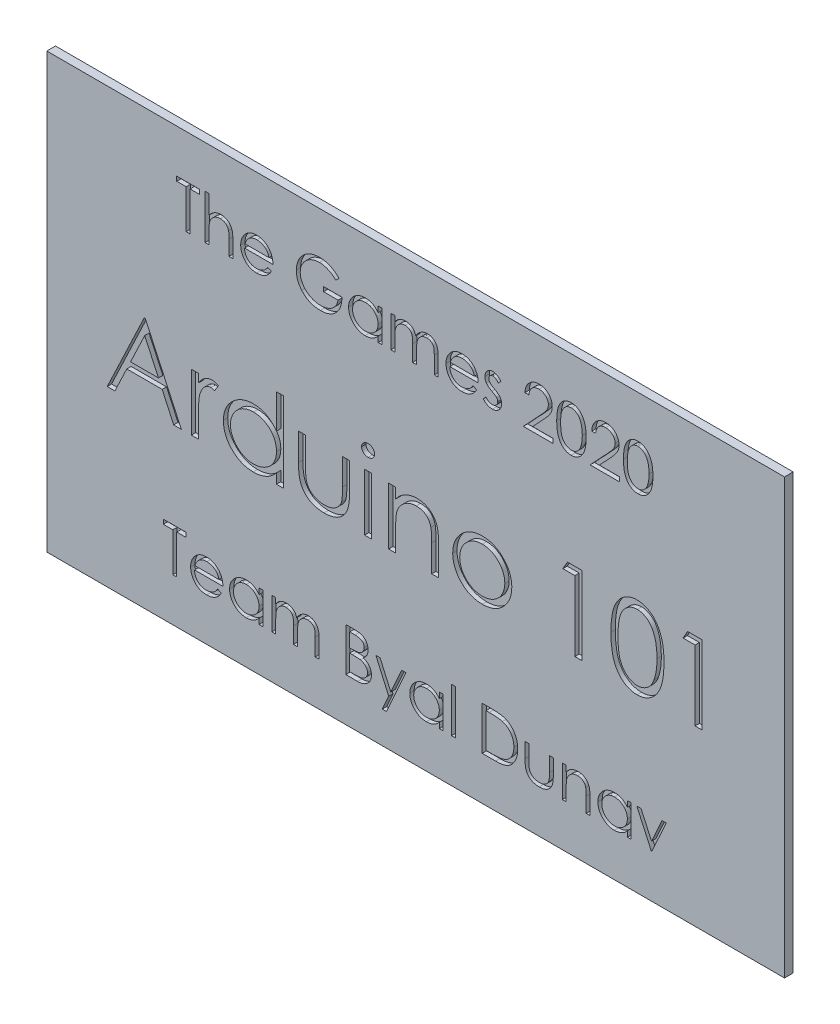
from build123d import *

# Parameters (mm, degrees)
SKETCH2_W           = 850
SKETCH2_H           = 500
BOSS_EXTRUDE1_DEPTH = 10
SKETCH3_R           = 20
BOSS_EXTRUDE2_DEPTH = 30
SKETCH4_W           = 4.487179487
SKETCH4_H           = 51.282051282
SKETCH4_W_2         = 8.076923077
SKETCH4_H_2         = 65.769230769
CUT_EXTRUDE3_DEPTH  = 5


with BuildPart() as part:
    # Sketch2 → Boss-Extrude1 (new body)
    with BuildSketch(Plane.XY):
        Rectangle(SKETCH2_W, SKETCH2_H)
    extrude(amount=BOSS_EXTRUDE1_DEPTH)

    # Sketch3 → Boss-Extrude2 (add)
    with BuildSketch(Plane(origin=(0, 0, 0), x_dir=(-1, 0, 0), z_dir=(0, 0, -1))):
        with Locations(Location((-350, 175, 0), (0, 0, 180))):
            Circle(SKETCH3_R)
        with Locations(Location((350, 175, 0), (0, 0, 180))):
            Circle(SKETCH3_R)
        with Locations(Location((350, -175, 0), (0, 0, 180))):
            Circle(SKETCH3_R)
        with Locations(Location((-350, -175, 0), (0, 0, 180))):
            Circle(SKETCH3_R)
    extrude(amount=BOSS_EXTRUDE2_DEPTH)

    # Sketch4 → Cut-Extrude3 (cut)
    # profile 1 of 36: a face of its own
    with BuildSketch(Plane.XY.offset(10)):
        Polygon((-290.705128205, -155.128205128), (-290.705128205, -150), (-264.423076923, -150), (-264.423076923, -155.128205128), (-275.320512821, -155.128205128), (-275.320512821, -200), (-279.807692308, -200), (-279.807692308, -155.128205128), align=None)
    # profile 2 of 36: a face of its own
    with BuildSketch(Plane.XY.offset(10)):
        with BuildLine():
            Line((-228.024839744, -188.461538462), (-224.038461538, -190.554887821))
            add(Edge.make_bspline(
                [(-224.038461538, -190.554887821), (-224.356127185, -191.118363982), (-224.974178735, -192.21466545), (-226.037046562, -193.720834886), (-227.151219027, -195.075802255), (-228.366989998, -196.243368745), (-229.647985412, -197.261245673), (-231.001309052, -198.151786026), (-232.434006448, -198.910622031), (-233.946145373, -199.549943858), (-235.550424675, -200.041508059), (-237.250732053, -200.388711215), (-239.050324844, -200.603329339), (-240.283841699, -200.628259921), (-240.915464744, -200.641025641)],
                knots=[0, 0, 0, 0, 1.120438281, 2.179929193, 3.190490725, 4.156257408, 5.095198341, 6.022838206, 6.959905092, 7.901321166, 8.864066838, 9.862729781, 10.905609505, 12, 12, 12, 12], degree=3))
            add(Edge.make_bspline(
                [(-240.915464744, -200.641025641), (-241.617492994, -200.624637422), (-242.986946732, -200.592668754), (-244.980371691, -200.31706212), (-246.857220525, -199.867456995), (-248.617387716, -199.239377831), (-250.256562753, -198.418987487), (-251.778003536, -197.419566319), (-253.189711048, -196.246248394), (-254.447199751, -194.88887063), (-255.579255218, -193.43627124), (-256.578195503, -191.922615748), (-257.413301661, -190.351712541), (-258.092624664, -188.733562198), (-258.641265592, -187.078363718), (-259.023647075, -185.371057039), (-259.244072046, -183.616262978), (-259.277849839, -182.429158182), (-259.294871795, -181.830929487)],
                knots=[0, 0, 0, 0, 1.145258523, 2.234067595, 3.276747158, 4.290159414, 5.277019952, 6.260822364, 7.254936242, 8.264827045, 9.274100331, 10.257902744, 11.220704747, 12.172965371, 13.118907548, 14.062713208, 15.023725156, 16, 16, 16, 16], degree=3))
            add(Edge.make_bspline(
                [(-259.294871795, -181.830929487), (-259.279741204, -181.269574767), (-259.249754372, -180.157043843), (-259.060743124, -178.510393207), (-258.725767509, -176.909986742), (-258.266105738, -175.354494628), (-257.672516507, -173.846521286), (-256.946341946, -172.385148948), (-256.086450835, -170.971932664), (-255.422555496, -170.080459326), (-255.088141026, -169.631410256)],
                knots=[0, 0, 0, 0, 1.024358464, 2.0301432, 3.019427413, 4.004406732, 4.986367066, 5.972626655, 6.978780325, 8, 8, 8, 8], degree=3))
            add(Edge.make_bspline(
                [(-255.088141026, -169.631410256), (-254.635174129, -169.090426398), (-253.743589177, -168.025595677), (-252.235641244, -166.626476738), (-250.602781296, -165.454422806), (-248.865472352, -164.48289229), (-247.003522722, -163.744697333), (-245.041961422, -163.194589016), (-242.958453047, -162.886331715), (-241.534092749, -162.842791235), (-240.805288462, -162.820512821)],
                knots=[0, 0, 0, 0, 1.030682036, 2.02871468, 2.997146059, 3.962720338, 4.930598197, 5.918074684, 6.934738563, 8, 8, 8, 8], degree=3))
            add(Edge.make_bspline(
                [(-240.805288462, -162.820512821), (-240.056036957, -162.839856376), (-238.586176301, -162.877804023), (-236.442860286, -163.229608786), (-234.41485005, -163.787502422), (-232.502957131, -164.575413715), (-230.706987692, -165.591978741), (-229.038615555, -166.851147905), (-227.469308233, -168.314263437), (-226.556328535, -169.439452143), (-226.091746795, -170.012019231)],
                knots=[0, 0, 0, 0, 1.056321875, 2.072262726, 3.055038591, 4.01806755, 4.982017516, 5.957941055, 6.960871419, 8, 8, 8, 8], degree=3))
            add(Edge.make_bspline(
                [(-226.091746795, -170.012019231), (-225.775647676, -170.443498965), (-225.145553489, -171.303586375), (-224.356309203, -172.706031476), (-223.67120356, -174.173325681), (-223.123589831, -175.729187068), (-222.680168386, -177.355181071), (-222.359356689, -179.062931709), (-222.171219281, -180.851930443), (-222.13423789, -182.070881236), (-222.115384615, -182.692307692)],
                knots=[0, 0, 0, 0, 0.94817472, 1.890038105, 2.849395472, 3.817997239, 4.812318967, 5.836947057, 6.897266129, 8, 8, 8, 8], degree=3))
            Line((-222.115384615, -182.692307692), (-254.807692308, -182.692307692))
            add(Edge.make_bspline(
                [(-254.807692308, -182.692307692), (-254.78569793, -183.173742896), (-254.742446874, -184.120465807), (-254.540801971, -185.505762708), (-254.222962346, -186.825381881), (-253.776261451, -188.069425338), (-253.235306519, -189.254141446), (-252.572653422, -190.370741974), (-251.782088366, -191.414140974), (-250.90029266, -192.393671511), (-249.918762727, -193.2659681), (-248.886152052, -194.04670776), (-247.787672552, -194.701073428), (-246.631985645, -195.23221471), (-245.420960143, -195.648019225), (-244.154214499, -195.931845235), (-242.834241408, -196.121946762), (-241.934445207, -196.143084836), (-241.476362179, -196.153846154)],
                knots=[0, 0, 0, 0, 1.094153842, 2.151609401, 3.174256925, 4.172055639, 5.149267565, 6.128595816, 7.11444997, 8.118368179, 9.117203808, 10.09244225, 11.054858984, 12.015122123, 12.976791628, 13.957293641, 14.960065497, 16, 16, 16, 16], degree=3))
            add(Edge.make_bspline(
                [(-241.476362179, -196.153846154), (-241.028488642, -196.14515963), (-240.139821629, -196.127923901), (-238.81638081, -195.960325173), (-237.514387561, -195.689321236), (-236.239230657, -195.319464235), (-235.016790002, -194.868366348), (-233.884710715, -194.32403981), (-232.843564777, -193.721900571), (-231.870465255, -193.033190927), (-230.926593921, -192.190216827), (-229.990272687, -191.138277956), (-228.986320496, -189.894170416), (-228.357897742, -188.957803759), (-228.024839744, -188.461538462)],
                knots=[0, 0, 0, 0, 0.99110716, 1.966546729, 2.947904876, 3.932708344, 4.903319531, 5.828989031, 6.710028674, 7.56322171, 8.463672341, 9.504779593, 10.677557249, 12, 12, 12, 12], degree=3))
        make_face()
        with BuildLine():
            add(Edge.make_bspline(
                [(-226.602564103, -178.205128205), (-226.766801596, -177.609944295), (-227.082905903, -176.464406858), (-227.743425395, -174.878108423), (-228.487304548, -173.468281266), (-229.367614996, -172.245715079), (-230.365025362, -171.159950608), (-231.5170994, -170.211113677), (-232.809040736, -169.362292948), (-234.234171317, -168.645828669), (-235.743339675, -168.035973545), (-237.323428132, -167.62704332), (-238.935682244, -167.346907001), (-240.026172049, -167.320819738), (-240.574919872, -167.307692308)],
                knots=[0, 0, 0, 0, 1.154881502, 2.222775134, 3.210006277, 4.132804581, 5.035138423, 5.962687519, 6.919655026, 7.923214229, 8.944639381, 9.960483929, 10.97369054, 12, 12, 12, 12], degree=3))
            add(Edge.make_bspline(
                [(-240.574919872, -167.307692308), (-241.022768993, -167.316430473), (-241.908072551, -167.333703988), (-243.212373526, -167.497562978), (-244.464940653, -167.768417905), (-245.67501619, -168.139345856), (-246.826742881, -168.633754463), (-247.943810999, -169.213514844), (-248.997816659, -169.921251755), (-249.656978023, -170.460663967), (-249.989983974, -170.733173077)],
                knots=[0, 0, 0, 0, 1.04873581, 2.073130211, 3.073294108, 4.04793562, 5.032784715, 6.005352987, 6.992311501, 8, 8, 8, 8], degree=3))
            add(Edge.make_bspline(
                [(-249.989983974, -170.733173077), (-250.228459431, -170.948806157), (-250.711075634, -171.385194958), (-251.355940227, -172.137040766), (-251.973375551, -172.947777368), (-252.535284876, -173.848422005), (-253.050678968, -174.828718848), (-253.532964357, -175.880399352), (-253.967055958, -177.01144407), (-254.211286101, -177.799621773), (-254.336939103, -178.205128205)],
                knots=[0, 0, 0, 0, 0.879870761, 1.780643979, 2.707998968, 3.669668524, 4.684282772, 5.740141944, 6.837334558, 8, 8, 8, 8], degree=3))
            Line((-254.336939103, -178.205128205), (-226.602564103, -178.205128205))
        make_face(mode=Mode.SUBTRACT)
    # profile 3 of 36: a face of its own
    with BuildSketch(Plane.XY.offset(10)):
        with BuildLine():
            Line((-175.961538462, -163.461538462), (-175.961538462, -200))
            Line((-175.961538462, -200), (-180.448717949, -200))
            Line((-180.448717949, -200), (-180.448717949, -193.679887821))
            add(Edge.make_bspline(
                [(-180.448717949, -193.679887821), (-180.954700672, -194.25188202), (-181.942132319, -195.368135893), (-183.591291147, -196.826452642), (-185.339407974, -198.031857236), (-187.177998276, -199.00542746), (-189.105401752, -199.736742551), (-191.117345856, -200.256544824), (-193.214651297, -200.590742469), (-194.646827794, -200.62411421), (-195.372596154, -200.641025641)],
                knots=[0, 0, 0, 0, 1.074387032, 2.096679803, 3.090159297, 4.057316773, 5.018401886, 5.985159533, 6.978961417, 8, 8, 8, 8], degree=3))
            add(Edge.make_bspline(
                [(-195.372596154, -200.641025641), (-196.017852637, -200.623506037), (-197.290326993, -200.588956603), (-199.162170952, -200.320923694), (-200.963488801, -199.890486242), (-202.695982696, -199.291902106), (-204.348441917, -198.497890369), (-205.935014726, -197.547301111), (-207.447481755, -196.415289252), (-208.862789455, -195.121174562), (-210.166103746, -193.715531888), (-211.309836212, -192.216309789), (-212.263451638, -190.629991162), (-213.060881363, -188.976660393), (-213.675114855, -187.243590114), (-214.10330963, -185.436773429), (-214.371030297, -183.558346664), (-214.40556545, -182.27921062), (-214.423076923, -181.630608974)],
                knots=[0, 0, 0, 0, 1.033919861, 2.038935746, 3.024066025, 3.998881131, 4.97069526, 5.957263378, 6.95902576, 7.993208707, 9.027059324, 10.027763471, 11.009749337, 11.988697705, 12.965288445, 13.950418724, 14.960734635, 16, 16, 16, 16], degree=3))
            add(Edge.make_bspline(
                [(-214.423076923, -181.630608974), (-214.405177332, -180.995413209), (-214.369790806, -179.739665447), (-214.106173379, -177.892826905), (-213.662873256, -176.113994609), (-213.040761146, -174.40889542), (-212.243018932, -172.775466132), (-211.272617689, -171.212551489), (-210.129487336, -169.715845811), (-208.811595808, -168.32054257), (-207.383956234, -167.031676652), (-205.856688649, -165.911547432), (-204.26778463, -164.944163877), (-202.592598766, -164.177685644), (-200.85592584, -163.557555579), (-199.042305186, -163.128513178), (-197.159282634, -162.875694303), (-195.880847033, -162.839083387), (-195.232371795, -162.820512821)],
                knots=[0, 0, 0, 0, 1.020392517, 2.01726096, 2.990465484, 3.961182959, 4.928053699, 5.906110375, 6.912531644, 7.948652711, 8.985773172, 9.998621852, 10.987621588, 11.969261332, 12.953316658, 13.946091881, 14.958173133, 16, 16, 16, 16], degree=3))
            add(Edge.make_bspline(
                [(-195.232371795, -162.820512821), (-194.486659523, -162.841052128), (-193.024352951, -162.881328741), (-190.88538139, -163.21651056), (-188.861888849, -163.782774377), (-186.938255249, -164.553024348), (-185.121388304, -165.576577621), (-183.428488528, -166.867719921), (-181.841838767, -168.418308307), (-180.922120315, -169.609314656), (-180.448717949, -170.222355769)],
                knots=[0, 0, 0, 0, 1.038897134, 2.037228247, 3.008116434, 3.962042015, 4.918381754, 5.904844433, 6.921570401, 8, 8, 8, 8], degree=3))
            Line((-180.448717949, -170.222355769), (-180.448717949, -163.461538462))
            Line((-180.448717949, -163.461538462), (-175.961538462, -163.461538462))
        make_face()
        with BuildLine():
            add(Edge.make_bspline(
                [(-195.172275641, -167.307692308), (-195.828194753, -167.33102999), (-197.122874753, -167.377094862), (-199.023503354, -167.736716221), (-200.842266412, -168.335067569), (-202.570067473, -169.153380443), (-204.179613425, -170.182362395), (-205.618094437, -171.426953585), (-206.897275885, -172.853196644), (-207.973108231, -174.454655364), (-208.85011533, -176.171485236), (-209.466787215, -177.966120066), (-209.873490749, -179.806191174), (-209.915041043, -181.054229543), (-209.935897436, -181.680689103)],
                knots=[0, 0, 0, 0, 1.031046209, 2.035121221, 3.029706178, 4.034933723, 5.034054252, 6.02443088, 7.017295772, 8.038157696, 9.050218397, 10.03989886, 11.016116709, 12, 12, 12, 12], degree=3))
            add(Edge.make_bspline(
                [(-209.935897436, -181.680689103), (-209.909256103, -182.303404919), (-209.856077862, -183.546395718), (-209.473925085, -185.388975386), (-208.832784036, -187.184033129), (-207.957897425, -188.916333037), (-206.862374215, -190.524677328), (-205.592536321, -191.97810765), (-204.136103731, -193.227958911), (-202.52285363, -194.274209963), (-200.799882624, -195.119388833), (-198.987969318, -195.707469397), (-197.121174487, -196.087151977), (-195.851855432, -196.131501646), (-195.212339744, -196.153846154)],
                knots=[0, 0, 0, 0, 0.979072187, 1.954306742, 2.945804271, 3.96968567, 4.997920485, 5.998718438, 6.996577872, 8.005894225, 9.015743152, 10.005417472, 10.995077863, 12, 12, 12, 12], degree=3))
            add(Edge.make_bspline(
                [(-195.212339744, -196.153846154), (-194.56310399, -196.130132383), (-193.271838468, -196.082968046), (-191.365571213, -195.721807113), (-189.515643173, -195.125109994), (-187.747254196, -194.297979612), (-186.099880894, -193.272874528), (-184.621339785, -192.072773228), (-183.371111665, -190.677013454), (-182.311217243, -189.143064125), (-181.480139861, -187.461464176), (-180.874767587, -185.670975736), (-180.516854647, -183.771536477), (-180.471744224, -182.473480378), (-180.448717949, -181.810897436)],
                knots=[0, 0, 0, 0, 1.01762866, 2.023962475, 3.030623092, 4.058876274, 5.077231937, 6.066672613, 7.034107872, 8.005628644, 8.981990164, 9.965428785, 10.961468474, 12, 12, 12, 12], degree=3))
            add(Edge.make_bspline(
                [(-180.448717949, -181.810897436), (-180.462427325, -181.306071286), (-180.489411717, -180.312413666), (-180.695562711, -178.85344913), (-181.023490231, -177.457253044), (-181.485578374, -176.122357486), (-182.092596723, -174.85614298), (-182.824707664, -173.649517834), (-183.694785517, -172.508757671), (-184.688824033, -171.449570943), (-185.776898355, -170.483478625), (-186.928248935, -169.621132329), (-188.156516749, -168.91272129), (-189.441045848, -168.326417412), (-190.784064912, -167.859858127), (-192.196502338, -167.548605359), (-193.663345008, -167.334886487), (-194.664002942, -167.316852476), (-195.172275641, -167.307692308)],
                knots=[0, 0, 0, 0, 1.050140795, 2.067009409, 3.05949893, 4.030605086, 5.00011959, 5.97591094, 6.962425594, 7.979863591, 8.993523472, 9.986985069, 10.967611495, 11.937549037, 12.921786183, 13.919465291, 14.943216303, 16, 16, 16, 16], degree=3))
        make_face(mode=Mode.SUBTRACT)
    # profile 4 of 36: a face of its own
    with BuildSketch(Plane.XY.offset(10)):
        with BuildLine():
            Line((-165.705128205, -163.461538462), (-161.217948718, -163.461538462))
            Line((-161.217948718, -163.461538462), (-161.217948718, -169.811698718))
            add(Edge.make_bspline(
                [(-161.217948718, -169.811698718), (-160.813892291, -169.25616155), (-160.039681439, -168.191699078), (-158.770172118, -166.788980732), (-157.501941939, -165.598578522), (-156.588607914, -164.973680357), (-156.149839744, -164.673477564)],
                knots=[0, 0, 0, 0, 1.134379233, 2.173579362, 3.122582517, 4, 4, 4, 4], degree=3))
            add(Edge.make_bspline(
                [(-156.149839744, -164.673477564), (-155.551773141, -164.387686632), (-154.366088859, -163.82109787), (-152.48867136, -163.246332742), (-150.567604653, -162.893117009), (-149.270344454, -162.844811674), (-148.617788462, -162.820512821)],
                knots=[0, 0, 0, 0, 1.014936303, 2.012140481, 3.000054389, 4, 4, 4, 4], degree=3))
            add(Edge.make_bspline(
                [(-148.617788462, -162.820512821), (-148.176459939, -162.835445546), (-147.303094524, -162.864996607), (-146.009036094, -163.057282823), (-144.753913068, -163.389656724), (-143.545141221, -163.852618495), (-142.406274374, -164.413285451), (-141.362142977, -165.071138421), (-140.424654289, -165.809668069), (-139.594282127, -166.662224255), (-138.847581765, -167.652747091), (-138.160741098, -168.807950647), (-137.526095207, -170.153774376), (-137.174362224, -171.130439247), (-136.989182692, -171.64463141)],
                knots=[0, 0, 0, 0, 1.009824226, 1.998387844, 2.986035974, 3.974953746, 4.955485308, 5.885931332, 6.793869504, 7.679848016, 8.601185859, 9.625726857, 10.749998409, 12, 12, 12, 12], degree=3))
            add(Edge.make_bspline(
                [(-136.989182692, -171.64463141), (-136.793307673, -171.291425421), (-136.407853143, -170.596365636), (-135.760629756, -169.612676175), (-135.082518378, -168.692579149), (-134.367739905, -167.835344515), (-133.618817236, -167.045205509), (-132.832225803, -166.319549771), (-132.012443212, -165.655261004), (-130.87255407, -164.879215868), (-129.389516822, -164.054913277), (-127.519686612, -163.34022122), (-125.57468416, -162.898562243), (-124.254431327, -162.846701203), (-123.587740385, -162.820512821)],
                knots=[0, 0, 0, 0, 0.86119277, 1.694706429, 2.50939023, 3.298075842, 4.073795165, 4.829715201, 5.57930267, 6.321991688, 7.768977793, 9.186738141, 10.579381044, 12, 12, 12, 12], degree=3))
            add(Edge.make_bspline(
                [(-123.587740385, -162.820512821), (-122.975148059, -162.843615976), (-121.776245398, -162.888831093), (-120.030855888, -163.243880712), (-118.403115812, -163.853561386), (-116.896300438, -164.685470479), (-115.536874532, -165.730887384), (-114.355212973, -166.974727921), (-113.358493496, -168.408193964), (-112.707370072, -169.756650946), (-112.26572344, -170.9471557), (-111.993420093, -171.961531291), (-111.75285302, -173.077982047), (-111.553120945, -174.297842925), (-111.407141629, -175.625423044), (-111.298988551, -177.058549842), (-111.2257875, -178.598337151), (-111.220615039, -179.66070144), (-111.217948718, -180.208333333)],
                knots=[0, 0, 0, 0, 1.209669288, 2.367440248, 3.500751976, 4.631527125, 5.755587489, 6.87532382, 8.007944318, 9.190864318, 9.82315674, 10.514484317, 11.263564316, 12.079023757, 12.955305781, 13.901327259, 14.918167583, 16, 16, 16, 16], degree=3))
            Line((-111.217948718, -180.208333333), (-111.217948718, -200))
            Line((-111.217948718, -200), (-115.705128205, -200))
            Line((-115.705128205, -200), (-115.705128205, -180.188301282))
            add(Edge.make_bspline(
                [(-115.705128205, -180.188301282), (-115.706240819, -179.720864512), (-115.708379094, -178.822522128), (-115.746859545, -177.533201396), (-115.819364031, -176.35793915), (-115.904144585, -175.298337891), (-116.021913291, -174.351926627), (-116.17399803, -173.520606361), (-116.335107742, -172.797837628), (-116.602764758, -171.996608376), (-117.030591781, -171.112748226), (-117.682270068, -170.159554287), (-118.503271586, -169.32982857), (-119.451273822, -168.609566901), (-120.530537318, -168.023943457), (-121.720033363, -167.605714746), (-123.012376957, -167.346816483), (-123.90698822, -167.321016261), (-124.368990385, -167.307692308)],
                knots=[0, 0, 0, 0, 1.253487763, 2.409012846, 3.458416907, 4.410876679, 5.259312806, 6.014470957, 6.676830364, 7.243083969, 8.276244668, 9.299465089, 10.325150304, 11.392391894, 12.482080715, 13.603491619, 14.762376348, 16, 16, 16, 16], degree=3))
            add(Edge.make_bspline(
                [(-124.368990385, -167.307692308), (-124.935704019, -167.327923128), (-126.055745607, -167.367906919), (-127.690681124, -167.776105104), (-129.261695647, -168.391537256), (-130.721911832, -169.283429501), (-132.065165983, -170.352120413), (-133.220874237, -171.622828924), (-134.175619747, -173.060399308), (-134.822105118, -174.391066484), (-135.230523707, -175.586344254), (-135.500193932, -176.630592426), (-135.709956667, -177.817471966), (-135.906678513, -179.13900755), (-136.035074627, -180.604295841), (-136.15176566, -182.206558712), (-136.206349414, -183.950615275), (-136.213984539, -185.15956797), (-136.217948718, -185.787259615)],
                knots=[0, 0, 0, 0, 1.090531906, 2.155305635, 3.229839962, 4.33261226, 5.44038871, 6.529323825, 7.629011124, 8.757537029, 9.370236727, 10.061839251, 10.834451254, 11.692844982, 12.636905849, 13.66920014, 14.789842145, 16, 16, 16, 16], degree=3))
            Line((-136.217948718, -185.787259615), (-136.217948718, -200))
            Line((-136.217948718, -200), (-140.705128205, -200))
            Line((-140.705128205, -200), (-140.705128205, -181.420272436))
            add(Edge.make_bspline(
                [(-140.705128205, -181.420272436), (-140.706262933, -180.896082168), (-140.708446036, -179.88759278), (-140.746679141, -178.441397418), (-140.819345165, -177.125953417), (-140.903352999, -175.942789648), (-141.024212692, -174.89405638), (-141.161495008, -173.974131265), (-141.323618015, -173.185320535), (-141.592044939, -172.320129323), (-142.002251628, -171.366973281), (-142.662083943, -170.350672978), (-143.485049377, -169.461128728), (-144.450347603, -168.701718036), (-145.536143063, -168.073982589), (-146.735905932, -167.62170042), (-148.038833258, -167.358496283), (-148.9370862, -167.32494633), (-149.399038462, -167.307692308)],
                knots=[0, 0, 0, 0, 1.320475261, 2.540461679, 3.643808994, 4.639130445, 5.527981419, 6.302341397, 6.981980563, 7.553956391, 8.582137848, 9.585246428, 10.591171744, 11.620968678, 12.668337649, 13.738356861, 14.836885341, 16, 16, 16, 16], degree=3))
            add(Edge.make_bspline(
                [(-149.399038462, -167.307692308), (-149.942127197, -167.329556022), (-151.02448376, -167.373129629), (-152.614511897, -167.765333541), (-154.150021663, -168.379677466), (-155.60651736, -169.231960596), (-156.944719479, -170.287661719), (-158.116266155, -171.529303087), (-159.101159377, -172.941432137), (-159.754471018, -174.258068087), (-160.175877791, -175.423400586), (-160.455811144, -176.41412841), (-160.696377227, -177.514131957), (-160.875148965, -178.726804972), (-161.047726331, -180.044249174), (-161.131016461, -181.473027598), (-161.212038777, -183.011914566), (-161.215930416, -184.074379498), (-161.217948718, -184.625400641)],
                knots=[0, 0, 0, 0, 1.098833095, 2.189935336, 3.297829714, 4.440610912, 5.596351641, 6.740013378, 7.886572111, 9.072425424, 9.705826452, 10.395263256, 11.156850408, 11.985370555, 12.878090359, 13.847760091, 14.883794034, 16, 16, 16, 16], degree=3))
            Line((-161.217948718, -184.625400641), (-161.217948718, -200))
            Line((-161.217948718, -200), (-165.705128205, -200))
            Line((-165.705128205, -200), (-165.705128205, -163.461538462))
        make_face()
    # profile 5 of 36: a face of its own
    with BuildSketch(Plane.XY.offset(10)):
        with BuildLine():
            Line((-80.448717949, -150), (-70.693108974, -150))
            add(Edge.make_bspline(
                [(-70.693108974, -150), (-70.215559286, -150.00251072), (-69.289949138, -150.00737712), (-67.943957112, -150.082850422), (-66.683259817, -150.185759992), (-65.507491641, -150.34904703), (-64.417195892, -150.546072418), (-63.409086789, -150.78466979), (-62.486370042, -151.070764271), (-61.384759522, -151.525711146), (-60.128750081, -152.201756408), (-58.768773043, -153.20073591), (-57.605855337, -154.422628241), (-56.603193663, -155.800951889), (-55.806034811, -157.3171772), (-55.229330564, -158.935165611), (-54.864218058, -160.634047639), (-54.826668998, -161.800378751), (-54.807692308, -162.389823718)],
                knots=[0, 0, 0, 0, 1.001505555, 1.941167018, 2.826882275, 3.653841531, 4.429895133, 5.150066043, 5.825578002, 6.45369114, 7.647487171, 8.808567382, 9.977351308, 11.170798116, 12.373658725, 13.556498008, 14.765093433, 16, 16, 16, 16], degree=3))
            add(Edge.make_bspline(
                [(-54.807692308, -162.389823718), (-54.823309714, -162.942003085), (-54.85399939, -164.027087614), (-55.147467381, -165.614146318), (-55.606905501, -167.124878015), (-56.245551918, -168.553769235), (-57.075580435, -169.868535138), (-58.059270702, -171.079781795), (-59.246082166, -172.136225467), (-60.135271308, -172.72683836), (-60.586939103, -173.026842949)],
                knots=[0, 0, 0, 0, 1.044552857, 2.05264487, 3.044412934, 4.028983338, 5.005914585, 5.980388656, 6.974128949, 8, 8, 8, 8], degree=3))
            add(Edge.make_bspline(
                [(-60.586939103, -173.026842949), (-60.018932994, -173.244914362), (-58.932196603, -173.662138996), (-57.43668214, -174.399788482), (-56.148184354, -175.202104345), (-55.056796554, -176.078273633), (-54.123401484, -177.022685215), (-53.308359461, -178.049186847), (-52.612911259, -179.171169103), (-52.017012351, -180.376933894), (-51.552030122, -181.654169156), (-51.203802917, -182.990894529), (-51.004267929, -184.382316746), (-50.975873054, -185.329250736), (-50.961538462, -185.807291667)],
                knots=[0, 0, 0, 0, 1.27268992, 2.434971085, 3.483601985, 4.442670788, 5.356604649, 6.2567628, 7.179492994, 8.113709626, 9.066344395, 10.018646069, 10.999752585, 12, 12, 12, 12], degree=3))
            add(Edge.make_bspline(
                [(-50.961538462, -185.807291667), (-50.975493405, -186.29538984), (-51.002950146, -187.25573667), (-51.205521172, -188.666524306), (-51.548508415, -190.014737829), (-52.020953363, -191.309097582), (-52.637557857, -192.547099503), (-53.387957348, -193.730146132), (-54.282693971, -194.846350855), (-55.283592099, -195.908116899), (-56.415908463, -196.862799575), (-57.637562105, -197.713023957), (-58.963938103, -198.412253415), (-60.373252303, -198.999625151), (-61.881313962, -199.448299415), (-63.48135121, -199.762193328), (-65.171984093, -199.973693856), (-66.332123395, -199.991082498), (-66.927083333, -200)],
                knots=[0, 0, 0, 0, 0.978564426, 1.925352924, 2.850884081, 3.763762016, 4.682927383, 5.618979971, 6.567305752, 7.547517671, 8.540179244, 9.531824382, 10.526200242, 11.540722885, 12.589160233, 13.674978461, 14.80764778, 16, 16, 16, 16], degree=3))
            Line((-66.927083333, -200), (-80.448717949, -200))
            Line((-80.448717949, -200), (-80.448717949, -150))
        make_face()
        with BuildLine():
            Line((-75.961538462, -155.128205128), (-75.961538462, -171.153846154))
            Line((-75.961538462, -171.153846154), (-72.946714744, -171.153846154))
            add(Edge.make_bspline(
                [(-72.946714744, -171.153846154), (-72.506017667, -171.148132968), (-71.654501106, -171.137093929), (-70.421359727, -171.105472256), (-69.27671661, -171.016928779), (-68.222547566, -170.92841075), (-67.260512652, -170.784488069), (-66.392743202, -170.613172027), (-65.605620389, -170.431987669), (-64.697912595, -170.123852142), (-63.668299046, -169.668456782), (-62.570683272, -168.961716266), (-61.603047992, -168.119939792), (-60.785945311, -167.148640338), (-60.117210017, -166.079123397), (-59.652728372, -164.928453677), (-59.33776717, -163.725308933), (-59.309316722, -162.899333893), (-59.294871795, -162.479967949)],
                knots=[0, 0, 0, 0, 1.156816544, 2.235205308, 3.236616184, 4.169592532, 5.011045266, 5.787822928, 6.49130361, 7.128639758, 8.301311294, 9.436451833, 10.541879658, 11.654887649, 12.756523258, 13.837046038, 14.901820046, 16, 16, 16, 16], degree=3))
            add(Edge.make_bspline(
                [(-59.294871795, -162.479967949), (-59.302388655, -162.202456927), (-59.317133796, -161.658088754), (-59.437895262, -160.864526552), (-59.643146325, -160.11818723), (-59.906779086, -159.408842797), (-60.275188924, -158.758673508), (-60.708952686, -158.145199284), (-61.233033976, -157.589311877), (-61.829567014, -157.069747615), (-62.515404483, -156.609111504), (-63.290137223, -156.20567203), (-64.164246896, -155.880803792), (-65.123001967, -155.596287328), (-66.18116036, -155.396454559), (-67.326511123, -155.229977592), (-68.56843568, -155.145224135), (-69.427651431, -155.134004666), (-69.871794872, -155.128205128)],
                knots=[0, 0, 0, 0, 0.91205012, 1.789085906, 2.630437955, 3.453916878, 4.269457761, 5.079663411, 5.91843418, 6.774407191, 7.675494373, 8.627863946, 9.638891023, 10.736472738, 11.911756761, 13.175263542, 14.539845004, 16, 16, 16, 16], degree=3))
            Line((-69.871794872, -155.128205128), (-75.961538462, -155.128205128))
        make_face(mode=Mode.SUBTRACT)
        with BuildLine():
            Line((-75.961538462, -176.282051282), (-75.961538462, -194.871794872))
            Line((-75.961538462, -194.871794872), (-69.571314103, -194.871794872))
            add(Edge.make_bspline(
                [(-69.571314103, -194.871794872), (-69.113900875, -194.866312766), (-68.232297181, -194.85574673), (-66.959422465, -194.821253094), (-65.77966384, -194.742792012), (-64.698404758, -194.619279874), (-63.70396972, -194.485302029), (-62.808288248, -194.305140873), (-62.00409977, -194.098727151), (-61.07160966, -193.779667548), (-60.021559541, -193.284003677), (-58.889975879, -192.536657586), (-57.883887048, -191.646324618), (-57.029526202, -190.615882986), (-56.329340652, -189.495435459), (-55.819977008, -188.307644745), (-55.505821912, -187.072137211), (-55.467790922, -186.229755603), (-55.448717949, -185.807291667)],
                knots=[0, 0, 0, 0, 1.160039823, 2.235823828, 3.228722157, 4.157150951, 4.99529583, 5.772374946, 6.472645482, 7.099169577, 8.269452708, 9.405989375, 10.527446681, 11.663510218, 12.788923519, 13.866172445, 14.929861265, 16, 16, 16, 16], degree=3))
            add(Edge.make_bspline(
                [(-55.448717949, -185.807291667), (-55.452662296, -185.543101088), (-55.460487369, -185.018981348), (-55.578496154, -184.24875536), (-55.750122865, -183.502671455), (-55.972000492, -182.778703734), (-56.295135736, -182.089941215), (-56.672372093, -181.422761793), (-57.114677831, -180.776283515), (-57.803880201, -179.958965609), (-58.806337123, -179.017293996), (-60.230719629, -178.095329678), (-61.850323886, -177.351789577), (-63.025002355, -177.036082772), (-63.631810897, -176.872996795)],
                knots=[0, 0, 0, 0, 0.723448775, 1.435228256, 2.130040452, 2.821711965, 3.505591119, 4.210454504, 4.921174351, 5.648778258, 7.137944449, 8.670945889, 10.280296675, 12, 12, 12, 12], degree=3))
            add(Edge.make_bspline(
                [(-63.631810897, -176.872996795), (-63.875083695, -176.823638453), (-64.4025493, -176.716619386), (-65.262657592, -176.603652194), (-66.244598576, -176.503008482), (-67.35063968, -176.428563372), (-68.582180267, -176.35161275), (-69.941850534, -176.321686734), (-71.424097886, -176.285983018), (-72.452560349, -176.283395386), (-72.986778846, -176.282051282)],
                knots=[0, 0, 0, 0, 0.634451884, 1.375622551, 2.216452059, 3.157844607, 4.20941857, 5.370758133, 6.634282058, 8, 8, 8, 8], degree=3))
            Line((-72.986778846, -176.282051282), (-75.961538462, -176.282051282))
        make_face(mode=Mode.SUBTRACT)
    # profile 6 of 36: a face of its own
    with BuildSketch(Plane.XY.offset(10)):
        Polygon((-45.833333333, -163.461538462), (-40.995592949, -163.461538462), (-28.625801282, -191.446314103), (-16.065705128, -163.461538462), (-11.217948718, -163.461538462), (-33.653846154, -213.461538462), (-38.501602564, -213.461538462), (-31.059695513, -196.885016026), align=None)
    # profile 7 of 36: a face of its own
    with BuildSketch(Plane.XY.offset(10)):
        with BuildLine():
            Line((31.730769231, -163.461538462), (31.730769231, -200))
            Line((31.730769231, -200), (27.243589744, -200))
            Line((27.243589744, -200), (27.243589744, -193.679887821))
            add(Edge.make_bspline(
                [(27.243589744, -193.679887821), (26.73760702, -194.25188202), (25.750175373, -195.368135893), (24.101016545, -196.826452642), (22.352899718, -198.031857236), (20.514309416, -199.00542746), (18.58690594, -199.736742551), (16.574961836, -200.256544824), (14.477656395, -200.590742469), (13.045479898, -200.62411421), (12.319711538, -200.641025641)],
                knots=[0, 0, 0, 0, 1.074387032, 2.096679803, 3.090159297, 4.057316773, 5.018401886, 5.985159533, 6.978961417, 8, 8, 8, 8], degree=3))
            add(Edge.make_bspline(
                [(12.319711538, -200.641025641), (11.674455055, -200.623506037), (10.4019807, -200.588956603), (8.53013674, -200.320923694), (6.728818891, -199.890486242), (4.996324996, -199.291902106), (3.343865775, -198.497890369), (1.757292966, -197.547301111), (0.244825937, -196.415289252), (-1.170481762, -195.121174562), (-2.473796054, -193.715531888), (-3.61752852, -192.216309789), (-4.571143946, -190.629991162), (-5.36857367, -188.976660393), (-5.982807162, -187.243590114), (-6.411001938, -185.436773429), (-6.678722605, -183.558346664), (-6.713257757, -182.27921062), (-6.730769231, -181.630608974)],
                knots=[0, 0, 0, 0, 1.033919861, 2.038935746, 3.024066025, 3.998881131, 4.97069526, 5.957263378, 6.95902576, 7.993208707, 9.027059324, 10.027763471, 11.009749337, 11.988697705, 12.965288445, 13.950418724, 14.960734635, 16, 16, 16, 16], degree=3))
            add(Edge.make_bspline(
                [(-6.730769231, -181.630608974), (-6.71286964, -180.995413209), (-6.677483113, -179.739665447), (-6.413865687, -177.892826905), (-5.970565563, -176.113994609), (-5.348453454, -174.40889542), (-4.55071124, -172.775466132), (-3.580309997, -171.212551489), (-2.437179644, -169.715845811), (-1.119288115, -168.32054257), (0.308351458, -167.031676652), (1.835619043, -165.911547432), (3.424523062, -164.944163877), (5.099708926, -164.177685644), (6.836381852, -163.557555579), (8.650002506, -163.128513178), (10.533025058, -162.875694303), (11.811460659, -162.839083387), (12.459935897, -162.820512821)],
                knots=[0, 0, 0, 0, 1.020392517, 2.01726096, 2.990465484, 3.961182959, 4.928053699, 5.906110375, 6.912531644, 7.948652711, 8.985773172, 9.998621852, 10.987621588, 11.969261332, 12.953316658, 13.946091881, 14.958173133, 16, 16, 16, 16], degree=3))
            add(Edge.make_bspline(
                [(12.459935897, -162.820512821), (13.20564817, -162.841052128), (14.667954741, -162.881328741), (16.806926302, -163.21651056), (18.830418843, -163.782774377), (20.754052444, -164.553024348), (22.570919388, -165.576577621), (24.263819164, -166.867719921), (25.850468925, -168.418308307), (26.770187378, -169.609314656), (27.243589744, -170.222355769)],
                knots=[0, 0, 0, 0, 1.038897134, 2.037228247, 3.008116434, 3.962042015, 4.918381754, 5.904844433, 6.921570401, 8, 8, 8, 8], degree=3))
            Line((27.243589744, -170.222355769), (27.243589744, -163.461538462))
            Line((27.243589744, -163.461538462), (31.730769231, -163.461538462))
        make_face()
        with BuildLine():
            add(Edge.make_bspline(
                [(12.520032051, -167.307692308), (11.864112939, -167.33102999), (10.569432939, -167.377094862), (8.668804338, -167.736716221), (6.85004128, -168.335067569), (5.122240219, -169.153380443), (3.512694267, -170.182362395), (2.074213255, -171.426953585), (0.795031807, -172.853196644), (-0.280800539, -174.454655364), (-1.157807638, -176.171485236), (-1.774479522, -177.966120066), (-2.181183057, -179.806191174), (-2.222733351, -181.054229543), (-2.243589744, -181.680689103)],
                knots=[0, 0, 0, 0, 1.031046209, 2.035121221, 3.029706178, 4.034933723, 5.034054252, 6.02443088, 7.017295772, 8.038157696, 9.050218397, 10.03989886, 11.016116709, 12, 12, 12, 12], degree=3))
            add(Edge.make_bspline(
                [(-2.243589744, -181.680689103), (-2.216948411, -182.303404919), (-2.16377017, -183.546395718), (-1.781617393, -185.388975386), (-1.140476343, -187.184033129), (-0.265589733, -188.916333037), (0.829933477, -190.524677328), (2.099771371, -191.97810765), (3.556203961, -193.227958911), (5.169454062, -194.274209963), (6.892425068, -195.119388833), (8.704338375, -195.707469397), (10.571133205, -196.087151977), (11.840452261, -196.131501646), (12.479967949, -196.153846154)],
                knots=[0, 0, 0, 0, 0.979072187, 1.954306742, 2.945804271, 3.96968567, 4.997920485, 5.998718438, 6.996577872, 8.005894225, 9.015743152, 10.005417472, 10.995077863, 12, 12, 12, 12], degree=3))
            add(Edge.make_bspline(
                [(12.479967949, -196.153846154), (13.129203702, -196.130132383), (14.420469224, -196.082968046), (16.32673648, -195.721807113), (18.17666452, -195.125109994), (19.945053496, -194.297979612), (21.592426799, -193.272874528), (23.070967907, -192.072773228), (24.321196027, -190.677013454), (25.38109045, -189.143064125), (26.212167831, -187.461464176), (26.817540105, -185.670975736), (27.175453045, -183.771536477), (27.220563468, -182.473480378), (27.243589744, -181.810897436)],
                knots=[0, 0, 0, 0, 1.01762866, 2.023962475, 3.030623092, 4.058876274, 5.077231937, 6.066672613, 7.034107872, 8.005628644, 8.981990164, 9.965428785, 10.961468474, 12, 12, 12, 12], degree=3))
            add(Edge.make_bspline(
                [(27.243589744, -181.810897436), (27.229880367, -181.306071286), (27.202895975, -180.312413666), (26.996744982, -178.85344913), (26.668817462, -177.457253044), (26.206729318, -176.122357486), (25.59971097, -174.85614298), (24.867600028, -173.649517834), (23.997522175, -172.508757671), (23.003483659, -171.449570943), (21.915409337, -170.483478625), (20.764058757, -169.621132329), (19.535790943, -168.91272129), (18.251261844, -168.326417412), (16.908242781, -167.859858127), (15.495805355, -167.548605359), (14.028962684, -167.334886487), (13.02830475, -167.316852476), (12.520032051, -167.307692308)],
                knots=[0, 0, 0, 0, 1.050140795, 2.067009409, 3.05949893, 4.030605086, 5.00011959, 5.97591094, 6.962425594, 7.979863591, 8.993523472, 9.986985069, 10.967611495, 11.937549037, 12.921786183, 13.919465291, 14.943216303, 16, 16, 16, 16], degree=3))
        make_face(mode=Mode.SUBTRACT)
    # profile 8 of 36: a face of its own
    with BuildSketch(Plane.XY.offset(10)):
        with Locations((43.58974359, -174.358974359)):
            Rectangle(SKETCH4_W, SKETCH4_H)
    # profile 9 of 36: a face of its own
    with BuildSketch(Plane.XY.offset(10)):
        with BuildLine():
            Line((76.602564103, -200), (76.602564103, -150))
            Line((76.602564103, -150), (86.698717949, -150))
            add(Edge.make_bspline(
                [(86.698717949, -150), (87.576846352, -150.006322429), (89.273385856, -150.018537327), (91.724992248, -150.095985772), (93.993331712, -150.232992427), (96.070943985, -150.432557086), (97.963532727, -150.677600424), (99.665798558, -150.984749057), (101.186543456, -151.347437206), (102.121821179, -151.656657923), (102.564102564, -151.802884615)],
                knots=[0, 0, 0, 0, 1.314313732, 2.53924729, 3.670748893, 4.714932338, 5.66265055, 6.526160246, 7.303039223, 8, 8, 8, 8], degree=3))
            add(Edge.make_bspline(
                [(102.564102564, -151.802884615), (103.14259884, -152.023323267), (104.286473015, -152.459201754), (105.915146195, -153.28143463), (107.448365666, -154.21305037), (108.89435345, -155.25527698), (110.220079541, -156.437624815), (111.477335209, -157.709868895), (112.614688406, -159.118273756), (113.656235492, -160.633630727), (114.595316342, -162.238088616), (115.411590025, -163.928590169), (116.089504216, -165.696550284), (116.652264596, -167.537052398), (117.095785418, -169.454143509), (117.398384442, -171.450055882), (117.597970012, -173.516901444), (117.618027888, -174.919393783), (117.628205128, -175.631009615)],
                knots=[0, 0, 0, 0, 0.984719456, 1.947108742, 2.898477687, 3.838006223, 4.779231079, 5.722358779, 6.681677486, 7.655904652, 8.64651281, 9.637519902, 10.640069247, 11.656948941, 12.698408672, 13.768548281, 14.867775369, 16, 16, 16, 16], degree=3))
            add(Edge.make_bspline(
                [(117.628205128, -175.631009615), (117.619219879, -176.249027308), (117.601513505, -177.466895722), (117.442523279, -179.261765659), (117.211432992, -181.003388107), (116.853658738, -182.683469536), (116.419337117, -184.316729791), (115.862706384, -185.885761853), (115.225056439, -187.40495913), (114.481486745, -188.853780214), (113.665181245, -190.226399819), (112.789156342, -191.520335935), (111.854346408, -192.717124818), (110.851837367, -193.820390704), (109.794584274, -194.828470395), (108.675665266, -195.7497849), (107.492193112, -196.566307112), (106.249468502, -197.310122944), (104.911238084, -197.958985166), (103.452154282, -198.507985306), (101.865994596, -198.962936954), (100.156652354, -199.34252118), (98.321174101, -199.643625503), (96.357760304, -199.845431109), (94.269427594, -199.981901576), (92.83543809, -199.993850053), (92.097355769, -200)],
                knots=[0, 0, 0, 0, 1.105936401, 2.179363191, 3.223086493, 4.248585256, 5.251745608, 6.245858792, 7.225916811, 8.198733463, 9.158002045, 10.082870192, 10.993790845, 11.873723703, 12.748670949, 13.606408763, 14.465103618, 15.319838547, 16.196477973, 17.123216899, 18.106603292, 19.147568657, 20.255746949, 21.433717677, 22.679120308, 24, 24, 24, 24], degree=3))
            Line((92.097355769, -200), (76.602564103, -200))
        make_face()
        with BuildLine():
            Line((81.08974359, -194.871794872), (86.828926282, -194.871794872))
            add(Edge.make_bspline(
                [(86.828926282, -194.871794872), (87.653617293, -194.868250638), (89.239800127, -194.861433778), (91.52062866, -194.80161659), (93.604620038, -194.703874626), (95.492070172, -194.5670878), (97.181913376, -194.386107583), (98.677681232, -194.184323258), (99.974470636, -193.932931105), (100.759176879, -193.705060256), (101.121794872, -193.599759615)],
                knots=[0, 0, 0, 0, 1.375205317, 2.645023457, 3.804390687, 4.853969522, 5.800190428, 6.637939096, 7.370582563, 8, 8, 8, 8], degree=3))
            add(Edge.make_bspline(
                [(101.121794872, -193.599759615), (101.578200044, -193.439023069), (102.480109161, -193.121389166), (103.778410378, -192.541994006), (104.989224731, -191.855678724), (106.133653663, -191.092789095), (107.195463027, -190.226417638), (108.187236117, -189.275403512), (109.106976136, -188.234906725), (109.945180536, -187.106218703), (110.695299165, -185.89636448), (111.344888157, -184.617238284), (111.914195751, -183.282855281), (112.361032788, -181.872724443), (112.711255419, -180.39945218), (112.95932239, -178.862934848), (113.113818454, -177.263459393), (113.131839139, -176.175571903), (113.141025641, -175.62099359)],
                knots=[0, 0, 0, 0, 0.998632004, 1.973411704, 2.929992603, 3.868527914, 4.809262121, 5.754881198, 6.702106254, 7.672490631, 8.653608572, 9.636854334, 10.631411391, 11.644891563, 12.686317036, 13.754757253, 14.855430412, 16, 16, 16, 16], degree=3))
            add(Edge.make_bspline(
                [(113.141025641, -175.62099359), (113.133692964, -175.036229585), (113.119287856, -173.887455523), (112.938226279, -172.201874162), (112.673632629, -170.580722012), (112.291008543, -169.023890649), (111.803424559, -167.528342761), (111.194929677, -166.102349758), (110.499692259, -164.730851631), (109.672501732, -163.445503549), (108.766564684, -162.229887705), (107.761166408, -161.116246053), (106.672280143, -160.102041764), (105.511782294, -159.171480154), (104.246966591, -158.36199907), (102.907628151, -157.637903626), (101.474118562, -157.023390893), (100.476794336, -156.696549996), (99.969951923, -156.530448718)],
                knots=[0, 0, 0, 0, 1.122418816, 2.205001699, 3.251619955, 4.274784885, 5.280384055, 6.268708349, 7.249350384, 8.229342522, 9.199999885, 10.157847722, 11.105861043, 12.055065948, 13.010012805, 13.98527497, 14.976112212, 16, 16, 16, 16], degree=3))
            add(Edge.make_bspline(
                [(99.969951923, -156.530448718), (99.550649832, -156.414499748), (98.659098542, -156.167960426), (97.204249056, -155.899026533), (95.566889779, -155.661819404), (93.739751191, -155.46099027), (91.724916061, -155.31688568), (89.520834804, -155.208724043), (87.126554739, -155.13577215), (85.466804256, -155.130790619), (84.60536859, -155.128205128)],
                knots=[0, 0, 0, 0, 0.674548936, 1.434276114, 2.292660221, 3.240891867, 4.284742987, 5.42552168, 6.663806718, 8, 8, 8, 8], degree=3))
            Line((84.60536859, -155.128205128), (81.08974359, -155.128205128))
            Line((81.08974359, -155.128205128), (81.08974359, -194.871794872))
        make_face(mode=Mode.SUBTRACT)
    # profile 10 of 36: a face of its own
    with BuildSketch(Plane.XY.offset(10)):
        with BuildLine():
            Line((125.961538462, -163.461538462), (130.448717949, -163.461538462))
            Line((130.448717949, -163.461538462), (130.448717949, -180.408653846))
            add(Edge.make_bspline(
                [(130.448717949, -180.408653846), (130.450745162, -180.906121692), (130.454623125, -181.857754378), (130.480922281, -183.227114189), (130.542780761, -184.475924369), (130.620121112, -185.604906323), (130.719580199, -186.61386906), (130.83791392, -187.499288446), (130.970177087, -188.271205361), (131.099644429, -188.736110443), (131.159855769, -188.952323718)],
                knots=[0, 0, 0, 0, 1.388932606, 2.656963016, 3.823490214, 4.879454478, 5.816252168, 6.653371382, 7.373723809, 8, 8, 8, 8], degree=3))
            add(Edge.make_bspline(
                [(131.159855769, -188.952323718), (131.256447984, -189.224079018), (131.447624284, -189.76193989), (131.794388338, -190.538925679), (132.223364574, -191.258572571), (132.692790687, -191.948630752), (133.234210796, -192.588659136), (133.840774669, -193.177576903), (134.492178055, -193.737635349), (135.46010696, -194.400275234), (136.78381076, -195.110494237), (138.521707264, -195.723291642), (140.406053349, -196.089517642), (141.708406481, -196.132007), (142.377804487, -196.153846154)],
                knots=[0, 0, 0, 0, 0.725840625, 1.436591201, 2.137033971, 2.831655856, 3.53531722, 4.242432219, 4.957935707, 5.694543706, 7.190802206, 8.724350549, 10.316345118, 12, 12, 12, 12], degree=3))
            add(Edge.make_bspline(
                [(142.377804487, -196.153846154), (143.047140312, -196.131542602), (144.342181288, -196.088389357), (146.205823706, -195.734338806), (147.90941534, -195.142828963), (149.435857502, -194.317008794), (150.778226647, -193.306407897), (151.896861201, -192.120567772), (152.81982198, -190.797005102), (153.222813703, -189.809515405), (153.425480769, -189.312900641)],
                knots=[0, 0, 0, 0, 1.157059328, 2.238695713, 3.266970494, 4.264342957, 5.228770407, 6.160125903, 7.074715775, 8, 8, 8, 8], degree=3))
            add(Edge.make_bspline(
                [(153.425480769, -189.312900641), (153.485398342, -189.113382089), (153.617861461, -188.672295297), (153.760180768, -187.924013177), (153.888387362, -187.031661684), (153.997861307, -185.98940156), (154.075935059, -184.799956525), (154.118021153, -183.463698294), (154.165567942, -181.98482172), (154.166289603, -180.949568016), (154.166666667, -180.408653846)],
                knots=[0, 0, 0, 0, 0.557542046, 1.232589297, 2.036731608, 2.971723315, 4.038036528, 5.22795436, 6.551621927, 8, 8, 8, 8], degree=3))
            Line((154.166666667, -180.408653846), (154.166666667, -163.461538462))
            Line((154.166666667, -163.461538462), (158.653846154, -163.461538462))
            Line((158.653846154, -163.461538462), (158.653846154, -181.25))
            add(Edge.make_bspline(
                [(158.653846154, -181.25), (158.647536228, -181.854388164), (158.635294108, -183.026983876), (158.556617773, -184.731042612), (158.421623306, -186.319074682), (158.216727807, -187.79192068), (157.975789598, -189.148456133), (157.664985699, -190.390419647), (157.293868016, -191.513984703), (156.875217802, -192.538867231), (156.380619695, -193.468108576), (155.854519402, -194.350048814), (155.247022661, -195.162805031), (154.607447886, -195.946835562), (153.895995659, -196.663143096), (153.125997674, -197.32816418), (152.308291676, -197.952064634), (151.424731705, -198.510511482), (150.48821652, -199.013606415), (149.497589992, -199.459550389), (148.440718589, -199.812444347), (147.33123806, -200.116882429), (146.163712641, -200.355660559), (144.939267883, -200.524040084), (143.658316222, -200.627259097), (142.785323941, -200.636359738), (142.337740385, -200.641025641)],
                knots=[0, 0, 0, 0, 1.493040784, 2.896703357, 4.213163133, 5.428574705, 6.569057535, 7.615249723, 8.588095153, 9.490268104, 10.346124644, 11.18633936, 12.024365274, 12.850166724, 13.684164916, 14.514361689, 15.362232829, 16.222528818, 17.093394965, 17.986930858, 18.902426812, 19.842810585, 20.827885679, 21.843828298, 22.894529745, 24, 24, 24, 24], degree=3))
            add(Edge.make_bspline(
                [(142.337740385, -200.641025641), (141.893504469, -200.636172682), (141.020539539, -200.626636165), (139.739521764, -200.524610341), (138.511684531, -200.355922189), (137.341393124, -200.115133369), (136.227473162, -199.814575227), (135.165412593, -199.457381863), (134.167647407, -199.013374981), (133.222190207, -198.513695589), (132.336441804, -197.948477368), (131.50631926, -197.328933945), (130.732935652, -196.655990187), (130.016120395, -195.932456514), (129.365935015, -195.149357423), (128.774277277, -194.312992276), (128.232038632, -193.431648153), (127.741284484, -192.487888689), (127.319687976, -191.451145692), (126.947470177, -190.304044305), (126.643032486, -189.034008351), (126.395282938, -187.642123659), (126.195976644, -186.135051636), (126.057603184, -184.504074274), (125.980234173, -182.753164387), (125.967904724, -181.543880243), (125.961538462, -180.919471154)],
                knots=[0, 0, 0, 0, 1.083640291, 2.129454052, 3.13281866, 4.105697902, 5.042300162, 5.946461698, 6.836384745, 7.703652036, 8.553297018, 9.397182691, 10.228592656, 11.052265423, 11.879314572, 12.708807002, 13.549817954, 14.402308542, 15.300838682, 16.27712199, 17.341985831, 18.484375296, 19.725102775, 21.0496083, 22.476576903, 24, 24, 24, 24], degree=3))
            Line((125.961538462, -180.919471154), (125.961538462, -163.461538462))
        make_face()
    # profile 11 of 36: a face of its own
    with BuildSketch(Plane.XY.offset(10)):
        with BuildLine():
            Line((168.91025641, -163.461538462), (173.397435897, -163.461538462))
            Line((173.397435897, -163.461538462), (173.397435897, -170.052083333))
            add(Edge.make_bspline(
                [(173.397435897, -170.052083333), (173.876544971, -169.45433015), (174.806272843, -168.294369243), (176.354620461, -166.769789606), (177.990961894, -165.513429249), (179.70527623, -164.511946478), (181.49989066, -163.756994676), (183.363865945, -163.211767089), (185.308361746, -162.884840967), (186.630710844, -162.842123391), (187.299679487, -162.820512821)],
                knots=[0, 0, 0, 0, 1.12780773, 2.188550248, 3.19190651, 4.159438251, 5.104880172, 6.052711206, 7.014878035, 8, 8, 8, 8], degree=3))
            add(Edge.make_bspline(
                [(187.299679487, -162.820512821), (187.975831403, -162.845444184), (189.2992238, -162.894240876), (191.226053248, -163.280193606), (193.025673158, -163.939411537), (194.691666812, -164.842441114), (196.193484146, -165.965390734), (197.512410595, -167.273644759), (198.603314129, -168.778445948), (199.334705029, -170.174491037), (199.816499996, -171.412902384), (200.119819104, -172.473570242), (200.377404553, -173.655258116), (200.600715239, -174.954395103), (200.751816837, -176.380083535), (200.870992431, -177.926479136), (200.956402349, -179.593081), (200.95979102, -180.745747106), (200.961538462, -181.340144231)],
                knots=[0, 0, 0, 0, 1.235846778, 2.418850247, 3.575807741, 4.728682307, 5.871620074, 6.994088408, 8.11269785, 9.256955736, 9.865816715, 10.540099792, 11.271859618, 12.076849838, 12.949306005, 13.892391288, 14.913166135, 16, 16, 16, 16], degree=3))
            Line((200.961538462, -181.340144231), (200.961538462, -200))
            Line((200.961538462, -200), (196.474358974, -200))
            Line((196.474358974, -200), (196.474358974, -182.8125))
            add(Edge.make_bspline(
                [(196.474358974, -182.8125), (196.47159886, -182.315036501), (196.46631923, -181.36347349), (196.449667135, -180.001058873), (196.409527041, -178.765536324), (196.35312257, -177.659859647), (196.270564991, -176.685090553), (196.184527401, -175.839243743), (196.079313446, -175.123393137), (195.985557544, -174.692463388), (195.943509615, -174.499198718)],
                knots=[0, 0, 0, 0, 1.430800155, 2.736877192, 3.918605307, 4.986035426, 5.920637409, 6.731861385, 7.431261377, 8, 8, 8, 8], degree=3))
            add(Edge.make_bspline(
                [(195.943509615, -174.499198718), (195.791716308, -173.931896076), (195.499561156, -172.84001401), (194.777647111, -171.358951829), (193.866015957, -170.098977718), (192.753189537, -169.067881694), (191.449917028, -168.26544117), (189.959814989, -167.708670388), (188.297262979, -167.360437971), (187.127914655, -167.325764657), (186.518429487, -167.307692308)],
                knots=[0, 0, 0, 0, 1.084156227, 2.086665306, 3.027808233, 3.945421172, 4.874247719, 5.839848303, 6.874090471, 8, 8, 8, 8], degree=3))
            add(Edge.make_bspline(
                [(186.518429487, -167.307692308), (186.157462579, -167.314492374), (185.443118393, -167.32794953), (184.38383308, -167.462968074), (183.356344892, -167.683803154), (182.350341906, -167.981926546), (181.385944853, -168.391387535), (180.432169264, -168.856092824), (179.524929777, -169.435352996), (178.644881246, -170.080933302), (177.826126851, -170.796350547), (177.064293445, -171.551272121), (176.38517887, -172.355209318), (175.769912081, -173.195208569), (175.238794032, -174.082806254), (174.775178489, -175.009439204), (174.38181142, -175.976327044), (174.186344385, -176.647399348), (174.088541667, -176.983173077)],
                knots=[0, 0, 0, 0, 1.023777757, 2.026029729, 3.023749952, 4.003683103, 4.997618607, 5.993177895, 7.010360494, 8.046726602, 9.087585522, 10.09234134, 11.086953743, 12.070360549, 13.043493632, 14.017870808, 15.008233677, 16, 16, 16, 16], degree=3))
            add(Edge.make_bspline(
                [(174.088541667, -176.983173077), (174.032260973, -177.229675978), (173.909740846, -177.766299898), (173.777409705, -178.64693446), (173.657301485, -179.665648389), (173.556773505, -180.821252918), (173.495267555, -182.117793991), (173.428204744, -183.549734531), (173.403789586, -185.122784365), (173.3996131, -186.217951404), (173.397435897, -186.788862179)],
                knots=[0, 0, 0, 0, 0.615963638, 1.340920617, 2.168419149, 3.115676021, 4.16674242, 5.331190069, 6.6087489, 8, 8, 8, 8], degree=3))
            Line((173.397435897, -186.788862179), (173.397435897, -200))
            Line((173.397435897, -200), (168.91025641, -200))
            Line((168.91025641, -200), (168.91025641, -163.461538462))
        make_face()
    # profile 12 of 36: a face of its own
    with BuildSketch(Plane.XY.offset(10)):
        with BuildLine():
            Line((248.397435897, -163.461538462), (248.397435897, -200))
            Line((248.397435897, -200), (243.91025641, -200))
            Line((243.91025641, -200), (243.91025641, -193.679887821))
            add(Edge.make_bspline(
                [(243.91025641, -193.679887821), (243.404273687, -194.25188202), (242.41684204, -195.368135893), (240.767683212, -196.826452642), (239.019566385, -198.031857236), (237.180976083, -199.00542746), (235.253572607, -199.736742551), (233.241628503, -200.256544824), (231.144323062, -200.590742469), (229.712146565, -200.62411421), (228.986378205, -200.641025641)],
                knots=[0, 0, 0, 0, 1.074387032, 2.096679803, 3.090159297, 4.057316773, 5.018401886, 5.985159533, 6.978961417, 8, 8, 8, 8], degree=3))
            add(Edge.make_bspline(
                [(228.986378205, -200.641025641), (228.341121722, -200.623506037), (227.068647366, -200.588956603), (225.196803407, -200.320923694), (223.395485558, -199.890486242), (221.662991663, -199.291902106), (220.010532442, -198.497890369), (218.423959633, -197.547301111), (216.911492604, -196.415289252), (215.496184904, -195.121174562), (214.192870613, -193.715531888), (213.049138147, -192.216309789), (212.095522721, -190.629991162), (211.298092996, -188.976660393), (210.683859504, -187.243590114), (210.255664729, -185.436773429), (209.987944062, -183.558346664), (209.953408909, -182.27921062), (209.935897436, -181.630608974)],
                knots=[0, 0, 0, 0, 1.033919861, 2.038935746, 3.024066025, 3.998881131, 4.97069526, 5.957263378, 6.95902576, 7.993208707, 9.027059324, 10.027763471, 11.009749337, 11.988697705, 12.965288445, 13.950418724, 14.960734635, 16, 16, 16, 16], degree=3))
            add(Edge.make_bspline(
                [(209.935897436, -181.630608974), (209.953797027, -180.995413209), (209.989183553, -179.739665447), (210.25280098, -177.892826905), (210.696101103, -176.113994609), (211.318213213, -174.40889542), (212.115955427, -172.775466132), (213.08635667, -171.212551489), (214.229487023, -169.715845811), (215.547378551, -168.32054257), (216.975018125, -167.031676652), (218.50228571, -165.911547432), (220.091189729, -164.944163877), (221.766375593, -164.177685644), (223.503048519, -163.557555579), (225.316669173, -163.128513178), (227.199691725, -162.875694303), (228.478127326, -162.839083387), (229.126602564, -162.820512821)],
                knots=[0, 0, 0, 0, 1.020392517, 2.01726096, 2.990465484, 3.961182959, 4.928053699, 5.906110375, 6.912531644, 7.948652711, 8.985773172, 9.998621852, 10.987621588, 11.969261332, 12.953316658, 13.946091881, 14.958173133, 16, 16, 16, 16], degree=3))
            add(Edge.make_bspline(
                [(229.126602564, -162.820512821), (229.872314836, -162.841052128), (231.334621408, -162.881328741), (233.473592969, -163.21651056), (235.49708551, -163.782774377), (237.42071911, -164.553024348), (239.237586055, -165.576577621), (240.930485831, -166.867719921), (242.517135592, -168.418308307), (243.436854044, -169.609314656), (243.91025641, -170.222355769)],
                knots=[0, 0, 0, 0, 1.038897134, 2.037228247, 3.008116434, 3.962042015, 4.918381754, 5.904844433, 6.921570401, 8, 8, 8, 8], degree=3))
            Line((243.91025641, -170.222355769), (243.91025641, -163.461538462))
            Line((243.91025641, -163.461538462), (248.397435897, -163.461538462))
        make_face()
        with BuildLine():
            add(Edge.make_bspline(
                [(229.186698718, -167.307692308), (228.530779605, -167.33102999), (227.236099606, -167.377094862), (225.335471005, -167.736716221), (223.516707947, -168.335067569), (221.788906886, -169.153380443), (220.179360934, -170.182362395), (218.740879922, -171.426953585), (217.461698474, -172.853196644), (216.385866128, -174.454655364), (215.508859029, -176.171485236), (214.892187144, -177.966120066), (214.48548361, -179.806191174), (214.443933316, -181.054229543), (214.423076923, -181.680689103)],
                knots=[0, 0, 0, 0, 1.031046209, 2.035121221, 3.029706178, 4.034933723, 5.034054252, 6.02443088, 7.017295772, 8.038157696, 9.050218397, 10.03989886, 11.016116709, 12, 12, 12, 12], degree=3))
            add(Edge.make_bspline(
                [(214.423076923, -181.680689103), (214.449718256, -182.303404919), (214.502896497, -183.546395718), (214.885049274, -185.388975386), (215.526190323, -187.184033129), (216.401076934, -188.916333037), (217.496600144, -190.524677328), (218.766438038, -191.97810765), (220.222870628, -193.227958911), (221.836120729, -194.274209963), (223.559091735, -195.119388833), (225.371005041, -195.707469397), (227.237799872, -196.087151977), (228.507118927, -196.131501646), (229.146634615, -196.153846154)],
                knots=[0, 0, 0, 0, 0.979072187, 1.954306742, 2.945804271, 3.96968567, 4.997920485, 5.998718438, 6.996577872, 8.005894225, 9.015743152, 10.005417472, 10.995077863, 12, 12, 12, 12], degree=3))
            add(Edge.make_bspline(
                [(229.146634615, -196.153846154), (229.795870369, -196.130132383), (231.087135891, -196.082968046), (232.993403146, -195.721807113), (234.843331186, -195.125109994), (236.611720163, -194.297979612), (238.259093465, -193.272874528), (239.737634574, -192.072773228), (240.987862694, -190.677013454), (242.047757116, -189.143064125), (242.878834498, -187.461464176), (243.484206772, -185.670975736), (243.842119711, -183.771536477), (243.887230135, -182.473480378), (243.91025641, -181.810897436)],
                knots=[0, 0, 0, 0, 1.01762866, 2.023962475, 3.030623092, 4.058876274, 5.077231937, 6.066672613, 7.034107872, 8.005628644, 8.981990164, 9.965428785, 10.961468474, 12, 12, 12, 12], degree=3))
            add(Edge.make_bspline(
                [(243.91025641, -181.810897436), (243.896547034, -181.306071286), (243.869562642, -180.312413666), (243.663411648, -178.85344913), (243.335484128, -177.457253044), (242.873395985, -176.122357486), (242.266377636, -174.85614298), (241.534266695, -173.649517834), (240.664188842, -172.508757671), (239.670150326, -171.449570943), (238.582076004, -170.483478625), (237.430725423, -169.621132329), (236.20245761, -168.91272129), (234.917928511, -168.326417412), (233.574909447, -167.859858127), (232.162472021, -167.548605359), (230.695629351, -167.334886487), (229.694971417, -167.316852476), (229.186698718, -167.307692308)],
                knots=[0, 0, 0, 0, 1.050140795, 2.067009409, 3.05949893, 4.030605086, 5.00011959, 5.97591094, 6.962425594, 7.979863591, 8.993523472, 9.986985069, 10.967611495, 11.937549037, 12.921786183, 13.919465291, 14.943216303, 16, 16, 16, 16], degree=3))
        make_face(mode=Mode.SUBTRACT)
    # profile 13 of 36: a face of its own
    with BuildSketch(Plane.XY.offset(10)):
        Polygon((254.807692308, -163.461538462), (259.665464744, -163.461538462), (271.794871795, -190.064102564), (283.924278846, -163.461538462), (288.782051282, -163.461538462), (272.115384615, -200), (271.474358974, -200), align=None)
    # profile 14 of 36: a face of its own
    with BuildSketch(Plane.XY.offset(10)):
        Polygon((-275.320512821, 194.871794872), (-275.320512821, 200), (-249.038461538, 200), (-249.038461538, 194.871794872), (-259.935897436, 194.871794872), (-259.935897436, 150), (-264.423076923, 150), (-264.423076923, 194.871794872), align=None)
    # profile 15 of 36: a face of its own
    with BuildSketch(Plane.XY.offset(10)):
        with BuildLine():
            Line((-242.628205128, 201.282051282), (-238.141025641, 201.282051282))
            Line((-238.141025641, 201.282051282), (-238.141025641, 179.637419872))
            add(Edge.make_bspline(
                [(-238.141025641, 179.637419872), (-237.659349903, 180.239476759), (-236.72150256, 181.411712368), (-235.142986608, 182.941157952), (-233.521974149, 184.266852541), (-231.802476866, 185.322144787), (-230.016040861, 186.155809691), (-228.155131655, 186.747061783), (-226.219403494, 187.110648878), (-224.904758493, 187.156340562), (-224.238782051, 187.179487179)],
                knots=[0, 0, 0, 0, 1.125788106, 2.19196713, 3.20547328, 4.180437432, 5.132270164, 6.079753143, 7.027236121, 8, 8, 8, 8], degree=3))
            add(Edge.make_bspline(
                [(-224.238782051, 187.179487179), (-223.562633582, 187.154552461), (-222.239247933, 187.105749203), (-220.312369894, 186.71984376), (-218.512928824, 186.060451788), (-216.846273927, 185.158065715), (-215.348778254, 184.034168183), (-214.022353051, 182.736575003), (-212.938913068, 181.232661886), (-212.201782826, 179.84328683), (-211.722162714, 178.607018916), (-211.418565194, 177.546497312), (-211.161148075, 176.364755695), (-210.936866135, 175.062402375), (-210.787386398, 173.633185642), (-210.667320427, 172.083553436), (-210.58194251, 170.413594606), (-210.578633874, 169.257591043), (-210.576923077, 168.659855769)],
                knots=[0, 0, 0, 0, 1.235656852, 2.418478516, 3.575258207, 4.727955599, 5.870717718, 6.98870536, 8.107142894, 9.245821548, 9.854588956, 10.528768408, 11.260415777, 12.065282286, 12.943670737, 13.886611085, 14.907229059, 16, 16, 16, 16], degree=3))
            Line((-210.576923077, 168.659855769), (-210.576923077, 150))
            Line((-210.576923077, 150), (-215.064102564, 150))
            Line((-215.064102564, 150), (-215.064102564, 167.1875))
            add(Edge.make_bspline(
                [(-215.064102564, 167.1875), (-215.066821181, 167.684966708), (-215.072021432, 168.636535856), (-215.089212068, 169.998908833), (-215.127586573, 171.234567898), (-215.189598371, 172.339552923), (-215.254817048, 173.315404399), (-215.344578722, 174.160705177), (-215.449010636, 174.876616253), (-215.542850371, 175.307539519), (-215.584935897, 175.500801282)],
                knots=[0, 0, 0, 0, 1.430932559, 2.737130458, 3.918967929, 4.986496826, 5.920444988, 6.731744033, 7.431208747, 8, 8, 8, 8], degree=3))
            add(Edge.make_bspline(
                [(-215.584935897, 175.500801282), (-215.748139399, 176.067862191), (-216.06189718, 177.158033487), (-216.791153997, 178.63892506), (-217.701997012, 179.901564213), (-218.814100749, 180.928911186), (-220.107791664, 181.73479032), (-221.591505437, 182.292901494), (-223.251277844, 182.639297522), (-224.420584583, 182.674144715), (-225.030048077, 182.692307692)],
                knots=[0, 0, 0, 0, 1.090059168, 2.095632401, 3.037101401, 3.955032261, 4.878929692, 5.839099886, 6.873700383, 8, 8, 8, 8], degree=3))
            add(Edge.make_bspline(
                [(-225.030048077, 182.692307692), (-225.391016265, 182.685510173), (-226.105362983, 182.672058059), (-227.164629638, 182.537002366), (-228.192187688, 182.316306386), (-229.197933086, 182.017670119), (-230.160550196, 181.611305312), (-231.108097696, 181.140874036), (-232.013729252, 180.565041822), (-232.893526636, 179.91895943), (-233.712348541, 179.203677148), (-234.474164476, 178.448720648), (-235.153283621, 177.644792587), (-235.768549207, 176.804790929), (-236.299667573, 175.91719388), (-236.763283032, 174.99056076), (-237.156650123, 174.023672965), (-237.352117155, 173.352600655), (-237.449919872, 173.016826923)],
                knots=[0, 0, 0, 0, 1.024319606, 2.027102035, 3.025350316, 4.005802111, 5.00026367, 5.987881639, 7.005602596, 8.042517216, 9.083927026, 10.089214625, 11.084353441, 12.06828073, 13.041928858, 14.016821737, 15.00770877, 16, 16, 16, 16], degree=3))
            add(Edge.make_bspline(
                [(-237.449919872, 173.016826923), (-237.506197404, 172.773670481), (-237.628833073, 172.243802667), (-237.76190212, 171.369883753), (-237.8810135, 170.354364153), (-237.981707068, 169.198784149), (-238.043465445, 167.898909259), (-238.110011742, 166.463609844), (-238.13478337, 164.883895261), (-238.138882697, 163.785388012), (-238.141025641, 163.211137821)],
                knots=[0, 0, 0, 0, 0.607992626, 1.324890765, 2.152360218, 3.099583803, 4.150613268, 5.323148443, 6.60066238, 8, 8, 8, 8], degree=3))
            Line((-238.141025641, 163.211137821), (-238.141025641, 150))
            Line((-238.141025641, 150), (-242.628205128, 150))
            Line((-242.628205128, 150), (-242.628205128, 201.282051282))
        make_face()
    # profile 16 of 36: a face of its own
    with BuildSketch(Plane.XY.offset(10)):
        with BuildLine():
            Line((-170.332532051, 161.538461538), (-166.346153846, 159.445112179))
            add(Edge.make_bspline(
                [(-166.346153846, 159.445112179), (-166.663819492, 158.881636018), (-167.281871042, 157.78533455), (-168.344738869, 156.279165114), (-169.458911335, 154.924197745), (-170.674682306, 153.756631255), (-171.95567772, 152.738754327), (-173.30900136, 151.848213974), (-174.741698756, 151.089377969), (-176.253837681, 150.450056142), (-177.858116983, 149.958491941), (-179.55842436, 149.611288785), (-181.358017152, 149.396670661), (-182.591534007, 149.371740079), (-183.223157051, 149.358974359)],
                knots=[0, 0, 0, 0, 1.120438281, 2.179929193, 3.190490725, 4.156257408, 5.095198341, 6.022838206, 6.959905092, 7.901321166, 8.864066838, 9.862729781, 10.905609505, 12, 12, 12, 12], degree=3))
            add(Edge.make_bspline(
                [(-183.223157051, 149.358974359), (-183.925185302, 149.375362578), (-185.29463904, 149.407331246), (-187.288063999, 149.68293788), (-189.164912833, 150.132543005), (-190.925080024, 150.760622169), (-192.56425506, 151.581012513), (-194.085695843, 152.580433681), (-195.497403356, 153.753751606), (-196.754892058, 155.11112937), (-197.886947526, 156.56372876), (-198.885887811, 158.077384252), (-199.720993969, 159.648287459), (-200.400316972, 161.266437802), (-200.9489579, 162.921636282), (-201.331339382, 164.628942961), (-201.551764353, 166.383737022), (-201.585542147, 167.570841818), (-201.602564103, 168.169070513)],
                knots=[0, 0, 0, 0, 1.145258523, 2.234067595, 3.276747158, 4.290159414, 5.277019952, 6.260822364, 7.254936242, 8.264827045, 9.274100331, 10.257902744, 11.220704747, 12.172965371, 13.118907548, 14.062713208, 15.023725156, 16, 16, 16, 16], degree=3))
            add(Edge.make_bspline(
                [(-201.602564103, 168.169070513), (-201.587433512, 168.730425233), (-201.55744668, 169.842956157), (-201.368435432, 171.489606793), (-201.033459816, 173.090013258), (-200.573798046, 174.645505372), (-199.980208814, 176.153478714), (-199.254034254, 177.614851052), (-198.394143143, 179.028067336), (-197.730247803, 179.919540674), (-197.395833333, 180.368589744)],
                knots=[0, 0, 0, 0, 1.024358464, 2.0301432, 3.019427413, 4.004406732, 4.986367066, 5.972626655, 6.978780325, 8, 8, 8, 8], degree=3))
            add(Edge.make_bspline(
                [(-197.395833333, 180.368589744), (-196.942866437, 180.909573602), (-196.051281485, 181.974404323), (-194.543333551, 183.373523262), (-192.910473604, 184.545577194), (-191.173164659, 185.51710771), (-189.31121503, 186.255302667), (-187.349653729, 186.805410984), (-185.266145355, 187.113668285), (-183.841785057, 187.157208765), (-183.112980769, 187.179487179)],
                knots=[0, 0, 0, 0, 1.030682036, 2.02871468, 2.997146059, 3.962720338, 4.930598197, 5.918074684, 6.934738563, 8, 8, 8, 8], degree=3))
            add(Edge.make_bspline(
                [(-183.112980769, 187.179487179), (-182.363729265, 187.160143624), (-180.893868609, 187.122195977), (-178.750552594, 186.770391214), (-176.722542358, 186.212497578), (-174.810649439, 185.424586285), (-173.014679999, 184.408021259), (-171.346307863, 183.148852095), (-169.777000541, 181.685736563), (-168.864020843, 180.560547857), (-168.399439103, 179.987980769)],
                knots=[0, 0, 0, 0, 1.056321875, 2.072262726, 3.055038591, 4.01806755, 4.982017516, 5.957941055, 6.960871419, 8, 8, 8, 8], degree=3))
            add(Edge.make_bspline(
                [(-168.399439103, 179.987980769), (-168.083339984, 179.556501035), (-167.453245797, 178.696413625), (-166.664001511, 177.293968524), (-165.978895868, 175.826674319), (-165.431282139, 174.270812932), (-164.987860693, 172.644818929), (-164.667048997, 170.937068291), (-164.478911589, 169.148069557), (-164.441930198, 167.929118764), (-164.423076923, 167.307692308)],
                knots=[0, 0, 0, 0, 0.94817472, 1.890038105, 2.849395472, 3.817997239, 4.812318967, 5.836947057, 6.897266129, 8, 8, 8, 8], degree=3))
            Line((-164.423076923, 167.307692308), (-197.115384615, 167.307692308))
            add(Edge.make_bspline(
                [(-197.115384615, 167.307692308), (-197.093390238, 166.826257104), (-197.050139181, 165.879534193), (-196.848494279, 164.494237292), (-196.530654654, 163.174618119), (-196.083953759, 161.930574662), (-195.542998827, 160.745858554), (-194.88034573, 159.629258026), (-194.089780673, 158.585859026), (-193.207984968, 157.606328489), (-192.226455034, 156.7340319), (-191.19384436, 155.95329224), (-190.09536486, 155.298926572), (-188.939677953, 154.76778529), (-187.728652451, 154.351980775), (-186.461906806, 154.068154765), (-185.141933716, 153.878053238), (-184.242137515, 153.856915164), (-183.784054487, 153.846153846)],
                knots=[0, 0, 0, 0, 1.094153842, 2.151609401, 3.174256925, 4.172055639, 5.149267565, 6.128595816, 7.11444997, 8.118368179, 9.117203808, 10.09244225, 11.054858984, 12.015122123, 12.976791628, 13.957293641, 14.960065497, 16, 16, 16, 16], degree=3))
            add(Edge.make_bspline(
                [(-183.784054487, 153.846153846), (-183.33618095, 153.85484037), (-182.447513937, 153.872076099), (-181.124073118, 154.039674827), (-179.822079869, 154.310678764), (-178.546922965, 154.680535765), (-177.324482309, 155.131633652), (-176.192403023, 155.67596019), (-175.151257085, 156.278099429), (-174.178157562, 156.966809073), (-173.234286229, 157.809783173), (-172.297964994, 158.861722044), (-171.294012803, 160.105829584), (-170.66559005, 161.042196241), (-170.332532051, 161.538461538)],
                knots=[0, 0, 0, 0, 0.99110716, 1.966546729, 2.947904876, 3.932708344, 4.903319531, 5.828989031, 6.710028674, 7.56322171, 8.463672341, 9.504779593, 10.677557249, 12, 12, 12, 12], degree=3))
        make_face()
        with BuildLine():
            add(Edge.make_bspline(
                [(-168.91025641, 171.794871795), (-169.074493904, 172.390055705), (-169.390598211, 173.535593142), (-170.051117703, 175.121891577), (-170.794996856, 176.531718734), (-171.675307304, 177.754284921), (-172.67271767, 178.840049392), (-173.824791708, 179.788886323), (-175.116733043, 180.637707052), (-176.541863625, 181.354171331), (-178.051031983, 181.964026455), (-179.63112044, 182.37295668), (-181.243374552, 182.653092999), (-182.333864357, 182.679180262), (-182.882612179, 182.692307692)],
                knots=[0, 0, 0, 0, 1.154881502, 2.222775134, 3.210006277, 4.132804581, 5.035138423, 5.962687519, 6.919655026, 7.923214229, 8.944639381, 9.960483929, 10.97369054, 12, 12, 12, 12], degree=3))
            add(Edge.make_bspline(
                [(-182.882612179, 182.692307692), (-183.330461301, 182.683569527), (-184.215764859, 182.666296012), (-185.520065833, 182.502437022), (-186.772632961, 182.231582095), (-187.982708498, 181.860654144), (-189.134435189, 181.366245537), (-190.251503306, 180.786485156), (-191.305508967, 180.078748245), (-191.964670331, 179.539336033), (-192.297676282, 179.266826923)],
                knots=[0, 0, 0, 0, 1.04873581, 2.073130211, 3.073294108, 4.04793562, 5.032784715, 6.005352987, 6.992311501, 8, 8, 8, 8], degree=3))
            add(Edge.make_bspline(
                [(-192.297676282, 179.266826923), (-192.536151739, 179.051193843), (-193.018767942, 178.614805042), (-193.663632535, 177.862959234), (-194.281067859, 177.052222632), (-194.842977184, 176.151577995), (-195.358371276, 175.171281152), (-195.840656664, 174.119600648), (-196.274748266, 172.98855593), (-196.518978409, 172.200378227), (-196.64463141, 171.794871795)],
                knots=[0, 0, 0, 0, 0.879870761, 1.780643979, 2.707998968, 3.669668524, 4.684282772, 5.740141944, 6.837334558, 8, 8, 8, 8], degree=3))
            Line((-196.64463141, 171.794871795), (-168.91025641, 171.794871795))
        make_face(mode=Mode.SUBTRACT)
    # profile 17 of 36: a face of its own
    with BuildSketch(Plane.XY.offset(10)):
        with BuildLine():
            Line((-88.141025641, 191.466346154), (-91.987179487, 187.820512821))
            add(Edge.make_bspline(
                [(-91.987179487, 187.820512821), (-92.683163603, 188.475239435), (-94.058535697, 189.769080334), (-96.300824877, 191.447808836), (-98.640305363, 192.885895981), (-101.064769604, 194.055985073), (-103.514177517, 194.989595937), (-105.956017178, 195.654283655), (-108.365241483, 196.078177047), (-109.967630317, 196.128868038), (-110.757211538, 196.153846154)],
                knots=[0, 0, 0, 0, 1.08915593, 2.152340314, 3.188132944, 4.216796309, 5.218260357, 6.173443236, 7.099959455, 8, 8, 8, 8], degree=3))
            add(Edge.make_bspline(
                [(-110.757211538, 196.153846154), (-111.241707252, 196.147937498), (-112.209442118, 196.136135511), (-113.646898461, 195.985503865), (-115.06927899, 195.76886295), (-116.47389863, 195.455407554), (-117.863488435, 195.058135275), (-119.233215466, 194.561200086), (-120.58563482, 193.981839454), (-121.908007406, 193.312375544), (-123.1900146, 192.576949166), (-124.400826537, 191.761970015), (-125.548160807, 190.893558731), (-126.610452597, 189.94997331), (-127.593812407, 188.939760948), (-128.521646292, 187.881713718), (-129.361321948, 186.746924881), (-130.119767161, 185.556273081), (-130.796361709, 184.330670377), (-131.393628189, 183.081913381), (-131.895015162, 181.814144032), (-132.291721666, 180.525771495), (-132.619016722, 179.226763067), (-132.849268253, 177.908124204), (-132.97907857, 176.568442984), (-133.001532569, 175.671339293), (-133.012820513, 175.220352564)],
                knots=[0, 0, 0, 0, 1.02818874, 2.053710826, 3.065248034, 4.081641283, 5.106893873, 6.131558223, 7.173050175, 8.228653731, 9.27666206, 10.308777013, 11.325269123, 12.329503258, 13.32196095, 14.316845687, 15.314881793, 16.315733098, 17.311955233, 18.285320748, 19.252783886, 20.203351036, 21.145449891, 22.095197417, 23.042428769, 24, 24, 24, 24], degree=3))
            add(Edge.make_bspline(
                [(-133.012820513, 175.220352564), (-133.002024538, 174.759340889), (-132.980462067, 173.83857641), (-132.842457502, 172.464375373), (-132.586339782, 171.11058391), (-132.243943941, 169.772753437), (-131.815646574, 168.448592753), (-131.281751344, 167.143842612), (-130.649385623, 165.858551309), (-129.917434879, 164.604299638), (-129.114774829, 163.382542163), (-128.215587958, 162.231691851), (-127.260436766, 161.136423605), (-126.214523911, 160.121055551), (-125.111387594, 159.158428461), (-123.918069365, 158.275063862), (-122.658034215, 157.453946386), (-121.32935976, 156.705424681), (-119.946462868, 156.036731314), (-118.528509252, 155.442104227), (-117.070969029, 154.952399408), (-115.581502034, 154.553283637), (-114.061883868, 154.226136533), (-112.504400972, 154.015672529), (-110.920505138, 153.862946373), (-109.852810394, 153.851779658), (-109.314903846, 153.846153846)],
                knots=[0, 0, 0, 0, 0.93586088, 1.869166235, 2.799637598, 3.729985548, 4.670839027, 5.622275134, 6.589130586, 7.576015415, 8.568469353, 9.55398029, 10.53834874, 11.515998671, 12.510579167, 13.508179873, 14.527009472, 15.561807829, 16.601455013, 17.643573243, 18.680854198, 19.719860599, 20.772568776, 21.833555941, 22.908541556, 24, 24, 24, 24], degree=3))
            add(Edge.make_bspline(
                [(-109.314903846, 153.846153846), (-108.666641743, 153.859704936), (-107.393673782, 153.886314704), (-105.522438886, 154.093461695), (-103.725252161, 154.416987319), (-102.007163544, 154.890785843), (-100.366177533, 155.495124057), (-98.796278372, 156.223629578), (-97.309826105, 157.104244707), (-95.902352197, 158.098157094), (-94.605820976, 159.205511844), (-93.436476346, 160.400432632), (-92.412969357, 161.677119299), (-91.520045082, 163.028052374), (-90.78135002, 164.464413875), (-90.175024376, 165.979164767), (-89.710263067, 167.572986366), (-89.519477712, 168.67429539), (-89.423076923, 169.230769231)],
                knots=[0, 0, 0, 0, 1.13008108, 2.219097802, 3.278683437, 4.311054135, 5.322181354, 6.324827112, 7.324222904, 8.330512327, 9.32562643, 10.293043162, 11.24128371, 12.174520618, 13.111833804, 14.052305215, 15.015860969, 16, 16, 16, 16], degree=3))
            Line((-89.423076923, 169.230769231), (-106.08974359, 169.230769231))
            Line((-106.08974359, 169.230769231), (-106.08974359, 174.358974359))
            Line((-106.08974359, 174.358974359), (-84.935897436, 174.358974359))
            add(Edge.make_bspline(
                [(-84.935897436, 174.358974359), (-84.960266698, 173.40315309), (-85.007961747, 171.532438208), (-85.342517685, 168.804291482), (-85.882753575, 166.227553006), (-86.62075803, 163.799509125), (-87.576119177, 161.523600657), (-88.738583869, 159.397516855), (-90.126757027, 157.434992842), (-91.691191906, 155.620007077), (-93.446905589, 154.001018331), (-95.346457303, 152.578076361), (-97.392985422, 151.37946757), (-99.5845541, 150.40431525), (-101.913988864, 149.64325818), (-104.386680004, 149.103664227), (-106.999274299, 148.780379036), (-108.789798255, 148.739073616), (-109.705528846, 148.717948718)],
                knots=[0, 0, 0, 0, 1.140356446, 2.231883559, 3.274166699, 4.278491846, 5.25512956, 6.21435461, 7.1637429, 8.11826594, 9.068280886, 10.0076534, 10.945064095, 11.891975133, 12.864533718, 13.863980011, 14.907571808, 16, 16, 16, 16], degree=3))
            add(Edge.make_bspline(
                [(-109.705528846, 148.717948718), (-110.269959351, 148.726079021), (-111.383198221, 148.7421146), (-113.027354336, 148.856076706), (-114.626177487, 149.03151351), (-116.179434757, 149.296443846), (-117.692839645, 149.620938905), (-119.158833716, 150.036463459), (-120.583001459, 150.517444878), (-121.967544111, 151.064525928), (-123.299894779, 151.698406737), (-124.585987879, 152.402830159), (-125.832932532, 153.174163884), (-127.032234889, 154.025747394), (-128.190143767, 154.951211111), (-129.299192962, 155.952409953), (-130.36559122, 157.026283092), (-131.033597842, 157.788840372), (-131.370192308, 158.173076923)],
                knots=[0, 0, 0, 0, 1.107784379, 2.184907829, 3.233506516, 4.263428166, 5.276301166, 6.270063455, 7.25232949, 8.225834625, 9.190232166, 10.146266622, 11.1027726, 12.066435141, 13.031522626, 14.010570082, 14.99756817, 16, 16, 16, 16], degree=3))
            add(Edge.make_bspline(
                [(-131.370192308, 158.173076923), (-131.858562764, 158.78265768), (-132.82719723, 159.991700783), (-134.074028039, 161.928842846), (-135.136905222, 163.934583705), (-135.999302681, 166.014506968), (-136.672703915, 168.166667151), (-137.155650383, 170.388314169), (-137.438611657, 172.682308891), (-137.479376477, 174.234669815), (-137.5, 175.020032051)],
                knots=[0, 0, 0, 0, 1.023165419, 2.029347347, 3.013907458, 3.994755782, 4.975994455, 5.96558838, 6.970761222, 8, 8, 8, 8], degree=3))
            add(Edge.make_bspline(
                [(-137.5, 175.020032051), (-137.492396598, 175.608121375), (-137.477286429, 176.776825768), (-137.294064769, 178.51193016), (-137.031187369, 180.216225762), (-136.644800875, 181.888319423), (-136.157711379, 183.529327877), (-135.549804436, 185.140013075), (-134.842020208, 186.721325527), (-134.019370263, 188.262380784), (-133.103877985, 189.742729538), (-132.110303409, 191.156412443), (-131.024537691, 192.4776848), (-129.864311983, 193.723279775), (-128.615783552, 194.877549018), (-127.290648928, 195.95117917), (-125.887886887, 196.945610396), (-124.403084316, 197.845179464), (-122.858403109, 198.653231185), (-121.257545946, 199.361648495), (-119.601001504, 199.94712443), (-117.901180395, 200.443892711), (-116.1452161, 200.811251862), (-114.345851288, 201.07766251), (-112.49370683, 201.259956791), (-111.241763554, 201.274617588), (-110.606971154, 201.282051282)],
                knots=[0, 0, 0, 0, 1.008945113, 2.00506715, 2.99143336, 3.967273523, 4.948097931, 5.927297278, 6.919902385, 7.919676788, 8.923139349, 9.905703106, 10.883022732, 11.856032218, 12.825136022, 13.798837087, 14.781400844, 15.773989409, 16.776158564, 17.77167057, 18.775803737, 19.789618931, 20.80898985, 21.851988756, 22.910860228, 24, 24, 24, 24], degree=3))
            add(Edge.make_bspline(
                [(-110.606971154, 201.282051282), (-110.089281959, 201.273772829), (-109.06276512, 201.257357628), (-107.535254658, 201.143576941), (-106.031354449, 200.963235783), (-104.548834593, 200.717138831), (-103.092743647, 200.381943253), (-101.65893357, 199.980824901), (-100.245325909, 199.513798864), (-98.856350921, 198.956815345), (-97.482669263, 198.324620703), (-96.116642971, 197.613000383), (-94.762939457, 196.809786031), (-93.419211151, 195.912592666), (-92.076984609, 194.936829554), (-90.757489719, 193.854589216), (-89.428876229, 192.708549847), (-88.574564598, 191.884518648), (-88.141025641, 191.466346154)],
                knots=[0, 0, 0, 0, 0.985871117, 1.954866573, 2.915460327, 3.869826059, 4.81536089, 5.759505086, 6.70452669, 7.649098992, 8.607881297, 9.583363685, 10.581137262, 11.603961102, 12.659522466, 13.73993555, 14.853081303, 16, 16, 16, 16], degree=3))
        make_face()
    # profile 18 of 36: a face of its own
    with BuildSketch(Plane.XY.offset(10)):
        with BuildLine():
            Line((-38.782051282, 186.538461538), (-38.782051282, 150))
            Line((-38.782051282, 150), (-43.269230769, 150))
            Line((-43.269230769, 150), (-43.269230769, 156.320112179))
            add(Edge.make_bspline(
                [(-43.269230769, 156.320112179), (-43.775213492, 155.74811798), (-44.762645139, 154.631864107), (-46.411803967, 153.173547358), (-48.159920795, 151.968142764), (-49.998511097, 150.99457254), (-51.925914573, 150.263257449), (-53.937858677, 149.743455176), (-56.035164118, 149.409257531), (-57.467340615, 149.37588579), (-58.193108974, 149.358974359)],
                knots=[0, 0, 0, 0, 1.074387032, 2.096679803, 3.090159297, 4.057316773, 5.018401886, 5.985159533, 6.978961417, 8, 8, 8, 8], degree=3))
            add(Edge.make_bspline(
                [(-58.193108974, 149.358974359), (-58.838365458, 149.376493963), (-60.110839813, 149.411043397), (-61.982683772, 149.679076306), (-63.784001622, 150.109513758), (-65.516495517, 150.708097894), (-67.168954737, 151.502109631), (-68.755527547, 152.452698889), (-70.267994576, 153.584710748), (-71.683302275, 154.878825438), (-72.986616566, 156.284468112), (-74.130349032, 157.783690211), (-75.083964459, 159.370008838), (-75.881394183, 161.023339607), (-76.495627675, 162.756409886), (-76.92382245, 164.563226571), (-77.191543118, 166.441653336), (-77.22607827, 167.72078938), (-77.243589744, 168.369391026)],
                knots=[0, 0, 0, 0, 1.033919861, 2.038935746, 3.024066025, 3.998881131, 4.97069526, 5.957263378, 6.95902576, 7.993208707, 9.027059324, 10.027763471, 11.009749337, 11.988697705, 12.965288445, 13.950418724, 14.960734635, 16, 16, 16, 16], degree=3))
            add(Edge.make_bspline(
                [(-77.243589744, 168.369391026), (-77.225690152, 169.004586791), (-77.190303626, 170.260334553), (-76.9266862, 172.107173095), (-76.483386076, 173.886005391), (-75.861273967, 175.59110458), (-75.063531753, 177.224533868), (-74.09313051, 178.787448511), (-72.950000157, 180.284154189), (-71.632108628, 181.67945743), (-70.204469054, 182.968323348), (-68.67720147, 184.088452568), (-67.088297451, 185.055836123), (-65.413111586, 185.822314356), (-63.67643866, 186.442444421), (-61.862818007, 186.871486822), (-59.979795454, 187.124305697), (-58.701359853, 187.160916613), (-58.052884615, 187.179487179)],
                knots=[0, 0, 0, 0, 1.020392517, 2.01726096, 2.990465484, 3.961182959, 4.928053699, 5.906110375, 6.912531644, 7.948652711, 8.985773172, 9.998621852, 10.987621588, 11.969261332, 12.953316658, 13.946091881, 14.958173133, 16, 16, 16, 16], degree=3))
            add(Edge.make_bspline(
                [(-58.052884615, 187.179487179), (-57.307172343, 187.158947872), (-55.844865772, 187.118671259), (-53.705894211, 186.78348944), (-51.682401669, 186.217225623), (-49.758768069, 185.446975652), (-47.941901125, 184.423422379), (-46.249001349, 183.132280079), (-44.662351587, 181.581691693), (-43.742633135, 180.390685344), (-43.269230769, 179.777644231)],
                knots=[0, 0, 0, 0, 1.038897134, 2.037228247, 3.008116434, 3.962042015, 4.918381754, 5.904844433, 6.921570401, 8, 8, 8, 8], degree=3))
            Line((-43.269230769, 179.777644231), (-43.269230769, 186.538461538))
            Line((-43.269230769, 186.538461538), (-38.782051282, 186.538461538))
        make_face()
        with BuildLine():
            add(Edge.make_bspline(
                [(-57.992788462, 182.692307692), (-58.648707574, 182.66897001), (-59.943387574, 182.622905138), (-61.844016174, 182.263283779), (-63.662779233, 181.664932431), (-65.390580294, 180.846619557), (-67.000126246, 179.817637605), (-68.438607257, 178.573046415), (-69.717788705, 177.146803356), (-70.793621052, 175.545344636), (-71.67062815, 173.828514764), (-72.287300035, 172.033879934), (-72.69400357, 170.193808826), (-72.735553863, 168.945770457), (-72.756410256, 168.319310897)],
                knots=[0, 0, 0, 0, 1.031046209, 2.035121221, 3.029706178, 4.034933723, 5.034054252, 6.02443088, 7.017295772, 8.038157696, 9.050218397, 10.03989886, 11.016116709, 12, 12, 12, 12], degree=3))
            add(Edge.make_bspline(
                [(-72.756410256, 168.319310897), (-72.729768923, 167.696595081), (-72.676590682, 166.453604282), (-72.294437905, 164.611024614), (-71.653296856, 162.815966871), (-70.778410246, 161.083666963), (-69.682887035, 159.475322672), (-68.413049142, 158.02189235), (-66.956616552, 156.772041089), (-65.343366451, 155.725790037), (-63.620395445, 154.880611167), (-61.808482138, 154.292530603), (-59.941687307, 153.912848023), (-58.672368252, 153.868498354), (-58.032852564, 153.846153846)],
                knots=[0, 0, 0, 0, 0.979072187, 1.954306742, 2.945804271, 3.96968567, 4.997920485, 5.998718438, 6.996577872, 8.005894225, 9.015743152, 10.005417472, 10.995077863, 12, 12, 12, 12], degree=3))
            add(Edge.make_bspline(
                [(-58.032852564, 153.846153846), (-57.38361681, 153.869867617), (-56.092351289, 153.917031954), (-54.186084033, 154.278192887), (-52.336155993, 154.874890006), (-50.567767016, 155.702020388), (-48.920393714, 156.727125472), (-47.441852605, 157.927226772), (-46.191624486, 159.322986546), (-45.131730063, 160.856935875), (-44.300652682, 162.538535824), (-43.695280408, 164.329024264), (-43.337367468, 166.228463523), (-43.292257045, 167.526519622), (-43.269230769, 168.189102564)],
                knots=[0, 0, 0, 0, 1.01762866, 2.023962475, 3.030623092, 4.058876274, 5.077231937, 6.066672613, 7.034107872, 8.005628644, 8.981990164, 9.965428785, 10.961468474, 12, 12, 12, 12], degree=3))
            add(Edge.make_bspline(
                [(-43.269230769, 168.189102564), (-43.282940146, 168.693928714), (-43.309924538, 169.687586334), (-43.516075531, 171.14655087), (-43.844003051, 172.542746956), (-44.306091194, 173.877642514), (-44.913109543, 175.14385702), (-45.645220484, 176.350482166), (-46.515298338, 177.491242329), (-47.509336853, 178.550429057), (-48.597411176, 179.516521375), (-49.748761756, 180.378867671), (-50.97702957, 181.08727871), (-52.261558668, 181.673582588), (-53.604577732, 182.140141873), (-55.017015158, 182.451394641), (-56.483857829, 182.665113513), (-57.484515763, 182.683147524), (-57.992788462, 182.692307692)],
                knots=[0, 0, 0, 0, 1.050140795, 2.067009409, 3.05949893, 4.030605086, 5.00011959, 5.97591094, 6.962425594, 7.979863591, 8.993523472, 9.986985069, 10.967611495, 11.937549037, 12.921786183, 13.919465291, 14.943216303, 16, 16, 16, 16], degree=3))
        make_face(mode=Mode.SUBTRACT)
    # profile 19 of 36: a face of its own
    with BuildSketch(Plane.XY.offset(10)):
        with BuildLine():
            Line((-28.525641026, 186.538461538), (-24.038461538, 186.538461538))
            Line((-24.038461538, 186.538461538), (-24.038461538, 180.188301282))
            add(Edge.make_bspline(
                [(-24.038461538, 180.188301282), (-23.634405111, 180.74383845), (-22.86019426, 181.808300922), (-21.590684938, 183.211019268), (-20.32245476, 184.401421478), (-19.409120735, 185.026319643), (-18.970352564, 185.326522436)],
                knots=[0, 0, 0, 0, 1.134379233, 2.173579362, 3.122582517, 4, 4, 4, 4], degree=3))
            add(Edge.make_bspline(
                [(-18.970352564, 185.326522436), (-18.372285961, 185.612313368), (-17.18660168, 186.17890213), (-15.309184181, 186.753667258), (-13.388117473, 187.106882991), (-12.090857274, 187.155188326), (-11.438301282, 187.179487179)],
                knots=[0, 0, 0, 0, 1.014936303, 2.012140481, 3.000054389, 4, 4, 4, 4], degree=3))
            add(Edge.make_bspline(
                [(-11.438301282, 187.179487179), (-10.99697276, 187.164554454), (-10.123607345, 187.135003393), (-8.829548915, 186.942717177), (-7.574425889, 186.610343276), (-6.365654041, 186.147381505), (-5.226787194, 185.586714549), (-4.182655798, 184.928861579), (-3.245167109, 184.190331931), (-2.414794948, 183.337775745), (-1.668094585, 182.347252909), (-0.981253919, 181.192049353), (-0.346608028, 179.846225624), (0.005124955, 178.869560753), (0.190304487, 178.35536859)],
                knots=[0, 0, 0, 0, 1.009824226, 1.998387844, 2.986035974, 3.974953746, 4.955485308, 5.885931332, 6.793869504, 7.679848016, 8.601185859, 9.625726857, 10.749998409, 12, 12, 12, 12], degree=3))
            add(Edge.make_bspline(
                [(0.190304487, 178.35536859), (0.386179507, 178.708574579), (0.771634037, 179.403634364), (1.418857424, 180.387323825), (2.096968802, 181.307420851), (2.811747274, 182.164655485), (3.560669943, 182.954794491), (4.347261376, 183.680450229), (5.167043968, 184.344738996), (6.30693311, 185.120784132), (7.789970358, 185.945086723), (9.659800568, 186.65977878), (11.604803019, 187.101437757), (12.925055852, 187.153298797), (13.591746795, 187.179487179)],
                knots=[0, 0, 0, 0, 0.86119277, 1.694706429, 2.50939023, 3.298075842, 4.073795165, 4.829715201, 5.57930267, 6.321991688, 7.768977793, 9.186738141, 10.579381044, 12, 12, 12, 12], degree=3))
            add(Edge.make_bspline(
                [(13.591746795, 187.179487179), (14.204339121, 187.156384024), (15.403241782, 187.111168907), (17.148631292, 186.756119288), (18.776371368, 186.146438614), (20.283186741, 185.314529521), (21.642612647, 184.269112616), (22.824274207, 183.025272079), (23.820993683, 181.591806036), (24.472117107, 180.243349054), (24.913763739, 179.0528443), (25.186067087, 178.038468709), (25.426634159, 176.922017953), (25.626366234, 175.702157075), (25.77234555, 174.374576956), (25.880498629, 172.941450158), (25.953699679, 171.401662849), (25.95887214, 170.33929856), (25.961538462, 169.791666667)],
                knots=[0, 0, 0, 0, 1.209669288, 2.367440248, 3.500751976, 4.631527125, 5.755587489, 6.87532382, 8.007944318, 9.190864318, 9.82315674, 10.514484317, 11.263564316, 12.079023757, 12.955305781, 13.901327259, 14.918167583, 16, 16, 16, 16], degree=3))
            Line((25.961538462, 169.791666667), (25.961538462, 150))
            Line((25.961538462, 150), (21.474358974, 150))
            Line((21.474358974, 150), (21.474358974, 169.811698718))
            add(Edge.make_bspline(
                [(21.474358974, 169.811698718), (21.47324636, 170.279135488), (21.471108086, 171.177477872), (21.432627635, 172.466798604), (21.360123148, 173.64206085), (21.275342594, 174.701662109), (21.157573889, 175.648073373), (21.00548915, 176.479393639), (20.844379437, 177.202162372), (20.576722421, 178.003391624), (20.148895398, 178.887251774), (19.497217112, 179.840445713), (18.676215594, 180.67017143), (17.728213357, 181.390433099), (16.648949862, 181.976056543), (15.459453816, 182.394285254), (14.167110222, 182.653183517), (13.272498959, 182.678983739), (12.810496795, 182.692307692)],
                knots=[0, 0, 0, 0, 1.253487763, 2.409012846, 3.458416907, 4.410876679, 5.259312806, 6.014470957, 6.676830364, 7.243083969, 8.276244668, 9.299465089, 10.325150304, 11.392391894, 12.482080715, 13.603491619, 14.762376348, 16, 16, 16, 16], degree=3))
            add(Edge.make_bspline(
                [(12.810496795, 182.692307692), (12.243783161, 182.672076872), (11.123741573, 182.632093081), (9.488806055, 182.223894896), (7.917791532, 181.608462744), (6.457575348, 180.716570499), (5.114321196, 179.647879587), (3.958612942, 178.377171076), (3.003867433, 176.939600692), (2.357382062, 175.608933516), (1.948963473, 174.413655746), (1.679293248, 173.369407574), (1.469530513, 172.182528034), (1.272808667, 170.86099245), (1.144412553, 169.395704159), (1.02772152, 167.793441288), (0.973137765, 166.049384725), (0.96550264, 164.84043203), (0.961538462, 164.212740385)],
                knots=[0, 0, 0, 0, 1.090531906, 2.155305635, 3.229839962, 4.33261226, 5.44038871, 6.529323825, 7.629011124, 8.757537029, 9.370236727, 10.061839251, 10.834451254, 11.692844982, 12.636905849, 13.66920014, 14.789842145, 16, 16, 16, 16], degree=3))
            Line((0.961538462, 164.212740385), (0.961538462, 150))
            Line((0.961538462, 150), (-3.525641026, 150))
            Line((-3.525641026, 150), (-3.525641026, 168.579727564))
            add(Edge.make_bspline(
                [(-3.525641026, 168.579727564), (-3.526775754, 169.103917832), (-3.528958857, 170.11240722), (-3.567191961, 171.558602582), (-3.639857986, 172.874046583), (-3.723865819, 174.057210352), (-3.844725513, 175.10594362), (-3.982007828, 176.025868735), (-4.144130836, 176.814679465), (-4.412557759, 177.679870677), (-4.822764449, 178.633026719), (-5.482596763, 179.649327022), (-6.305562197, 180.538871272), (-7.270860424, 181.298281964), (-8.356655884, 181.926017411), (-9.556418752, 182.37829958), (-10.859346079, 182.641503717), (-11.75759902, 182.67505367), (-12.219551282, 182.692307692)],
                knots=[0, 0, 0, 0, 1.320475261, 2.540461679, 3.643808994, 4.639130445, 5.527981419, 6.302341397, 6.981980563, 7.553956391, 8.582137848, 9.585246428, 10.591171744, 11.620968678, 12.668337649, 13.738356861, 14.836885341, 16, 16, 16, 16], degree=3))
            add(Edge.make_bspline(
                [(-12.219551282, 182.692307692), (-12.762640017, 182.670443978), (-13.84499658, 182.626870371), (-15.435024718, 182.234666459), (-16.970534484, 181.620322534), (-18.427030181, 180.768039404), (-19.7652323, 179.712338281), (-20.936778975, 178.470696913), (-21.921672197, 177.058567863), (-22.574983839, 175.741931913), (-22.996390612, 174.576599414), (-23.276323964, 173.58587159), (-23.516890047, 172.485868043), (-23.695661786, 171.273195028), (-23.868239152, 169.955750826), (-23.951529281, 168.526972402), (-24.032551598, 166.988085434), (-24.036443236, 165.925620502), (-24.038461538, 165.374599359)],
                knots=[0, 0, 0, 0, 1.098833095, 2.189935336, 3.297829714, 4.440610912, 5.596351641, 6.740013378, 7.886572111, 9.072425424, 9.705826452, 10.395263256, 11.156850408, 11.985370555, 12.878090359, 13.847760091, 14.883794034, 16, 16, 16, 16], degree=3))
            Line((-24.038461538, 165.374599359), (-24.038461538, 150))
            Line((-24.038461538, 150), (-28.525641026, 150))
            Line((-28.525641026, 150), (-28.525641026, 186.538461538))
        make_face()
    # profile 20 of 36: a face of its own
    with BuildSketch(Plane.XY.offset(10)):
        with BuildLine():
            Line((66.205929487, 161.538461538), (70.192307692, 159.445112179))
            add(Edge.make_bspline(
                [(70.192307692, 159.445112179), (69.874642046, 158.881636018), (69.256590496, 157.78533455), (68.193722669, 156.279165114), (67.079550204, 154.924197745), (65.863779232, 153.756631255), (64.582783819, 152.738754327), (63.229460179, 151.848213974), (61.796762783, 151.089377969), (60.284623857, 150.450056142), (58.680344555, 149.958491941), (56.980037178, 149.611288785), (55.180444387, 149.396670661), (53.946927532, 149.371740079), (53.315304487, 149.358974359)],
                knots=[0, 0, 0, 0, 1.120438281, 2.179929193, 3.190490725, 4.156257408, 5.095198341, 6.022838206, 6.959905092, 7.901321166, 8.864066838, 9.862729781, 10.905609505, 12, 12, 12, 12], degree=3))
            add(Edge.make_bspline(
                [(53.315304487, 149.358974359), (52.613276237, 149.375362578), (51.243822499, 149.407331246), (49.25039754, 149.68293788), (47.373548706, 150.132543005), (45.613381515, 150.760622169), (43.974206478, 151.581012513), (42.452765695, 152.580433681), (41.041058183, 153.753751606), (39.78356948, 155.11112937), (38.651514013, 156.56372876), (37.652573727, 158.077384252), (36.81746757, 159.648287459), (36.138144567, 161.266437802), (35.589503639, 162.921636282), (35.207122156, 164.628942961), (34.986697185, 166.383737022), (34.952919392, 167.570841818), (34.935897436, 168.169070513)],
                knots=[0, 0, 0, 0, 1.145258523, 2.234067595, 3.276747158, 4.290159414, 5.277019952, 6.260822364, 7.254936242, 8.264827045, 9.274100331, 10.257902744, 11.220704747, 12.172965371, 13.118907548, 14.062713208, 15.023725156, 16, 16, 16, 16], degree=3))
            add(Edge.make_bspline(
                [(34.935897436, 168.169070513), (34.951028026, 168.730425233), (34.981014858, 169.842956157), (35.170026107, 171.489606793), (35.505001722, 173.090013258), (35.964663493, 174.645505372), (36.558252724, 176.153478714), (37.284427284, 177.614851052), (38.144318396, 179.028067336), (38.808213735, 179.919540674), (39.142628205, 180.368589744)],
                knots=[0, 0, 0, 0, 1.024358464, 2.0301432, 3.019427413, 4.004406732, 4.986367066, 5.972626655, 6.978780325, 8, 8, 8, 8], degree=3))
            add(Edge.make_bspline(
                [(39.142628205, 180.368589744), (39.595595102, 180.909573602), (40.487180053, 181.974404323), (41.995127987, 183.373523262), (43.627987935, 184.545577194), (45.365296879, 185.51710771), (47.227246509, 186.255302667), (49.188807809, 186.805410984), (51.272316184, 187.113668285), (52.696676481, 187.157208765), (53.425480769, 187.179487179)],
                knots=[0, 0, 0, 0, 1.030682036, 2.02871468, 2.997146059, 3.962720338, 4.930598197, 5.918074684, 6.934738563, 8, 8, 8, 8], degree=3))
            add(Edge.make_bspline(
                [(53.425480769, 187.179487179), (54.174732274, 187.160143624), (55.64459293, 187.122195977), (57.787908945, 186.770391214), (59.815919181, 186.212497578), (61.7278121, 185.424586285), (63.523781539, 184.408021259), (65.192153676, 183.148852095), (66.761460998, 181.685736563), (67.674440696, 180.560547857), (68.139022436, 179.987980769)],
                knots=[0, 0, 0, 0, 1.056321875, 2.072262726, 3.055038591, 4.01806755, 4.982017516, 5.957941055, 6.960871419, 8, 8, 8, 8], degree=3))
            add(Edge.make_bspline(
                [(68.139022436, 179.987980769), (68.455121555, 179.556501035), (69.085215742, 178.696413625), (69.874460028, 177.293968524), (70.559565671, 175.826674319), (71.107179399, 174.270812932), (71.550600845, 172.644818929), (71.871412541, 170.937068291), (72.05954995, 169.148069557), (72.09653134, 167.929118764), (72.115384615, 167.307692308)],
                knots=[0, 0, 0, 0, 0.94817472, 1.890038105, 2.849395472, 3.817997239, 4.812318967, 5.836947057, 6.897266129, 8, 8, 8, 8], degree=3))
            Line((72.115384615, 167.307692308), (39.423076923, 167.307692308))
            add(Edge.make_bspline(
                [(39.423076923, 167.307692308), (39.445071301, 166.826257104), (39.488322357, 165.879534193), (39.689967259, 164.494237292), (40.007806885, 163.174618119), (40.45450778, 161.930574662), (40.995462712, 160.745858554), (41.658115809, 159.629258026), (42.448680865, 158.585859026), (43.330476571, 157.606328489), (44.312006504, 156.7340319), (45.344617179, 155.95329224), (46.443096679, 155.298926572), (47.598783586, 154.76778529), (48.809809088, 154.351980775), (50.076554732, 154.068154765), (51.396527823, 153.878053238), (52.296324023, 153.856915164), (52.754407051, 153.846153846)],
                knots=[0, 0, 0, 0, 1.094153842, 2.151609401, 3.174256925, 4.172055639, 5.149267565, 6.128595816, 7.11444997, 8.118368179, 9.117203808, 10.09244225, 11.054858984, 12.015122123, 12.976791628, 13.957293641, 14.960065497, 16, 16, 16, 16], degree=3))
            add(Edge.make_bspline(
                [(52.754407051, 153.846153846), (53.202280588, 153.85484037), (54.090947602, 153.872076099), (55.414388421, 154.039674827), (56.716381669, 154.310678764), (57.991538573, 154.680535765), (59.213979229, 155.131633652), (60.346058516, 155.67596019), (61.387204453, 156.278099429), (62.360303976, 156.966809073), (63.30417531, 157.809783173), (64.240496544, 158.861722044), (65.244448735, 160.105829584), (65.872871489, 161.042196241), (66.205929487, 161.538461538)],
                knots=[0, 0, 0, 0, 0.99110716, 1.966546729, 2.947904876, 3.932708344, 4.903319531, 5.828989031, 6.710028674, 7.56322171, 8.463672341, 9.504779593, 10.677557249, 12, 12, 12, 12], degree=3))
        make_face()
        with BuildLine():
            add(Edge.make_bspline(
                [(67.628205128, 171.794871795), (67.463967635, 172.390055705), (67.147863328, 173.535593142), (66.487343836, 175.121891577), (65.743464683, 176.531718734), (64.863154235, 177.754284921), (63.865743868, 178.840049392), (62.713669831, 179.788886323), (61.421728495, 180.637707052), (59.996597914, 181.354171331), (58.487429556, 181.964026455), (56.907341099, 182.37295668), (55.295086987, 182.653092999), (54.204597182, 182.679180262), (53.655849359, 182.692307692)],
                knots=[0, 0, 0, 0, 1.154881502, 2.222775134, 3.210006277, 4.132804581, 5.035138423, 5.962687519, 6.919655026, 7.923214229, 8.944639381, 9.960483929, 10.97369054, 12, 12, 12, 12], degree=3))
            add(Edge.make_bspline(
                [(53.655849359, 182.692307692), (53.208000237, 182.683569527), (52.322696679, 182.666296012), (51.018395705, 182.502437022), (49.765828578, 182.231582095), (48.555753041, 181.860654144), (47.404026349, 181.366245537), (46.286958232, 180.786485156), (45.232952571, 180.078748245), (44.573791207, 179.539336033), (44.240785256, 179.266826923)],
                knots=[0, 0, 0, 0, 1.04873581, 2.073130211, 3.073294108, 4.04793562, 5.032784715, 6.005352987, 6.992311501, 8, 8, 8, 8], degree=3))
            add(Edge.make_bspline(
                [(44.240785256, 179.266826923), (44.0023098, 179.051193843), (43.519693597, 178.614805042), (42.874829004, 177.862959234), (42.25739368, 177.052222632), (41.695484355, 176.151577995), (41.180090262, 175.171281152), (40.697804874, 174.119600648), (40.263713273, 172.98855593), (40.01948313, 172.200378227), (39.893830128, 171.794871795)],
                knots=[0, 0, 0, 0, 0.879870761, 1.780643979, 2.707998968, 3.669668524, 4.684282772, 5.740141944, 6.837334558, 8, 8, 8, 8], degree=3))
            Line((39.893830128, 171.794871795), (67.628205128, 171.794871795))
        make_face(mode=Mode.SUBTRACT)
    # profile 21 of 36: a face of its own
    with BuildSketch(Plane.XY.offset(10)):
        with BuildLine():
            Line((98.397435897, 181.981169872), (95.352564103, 178.846153846))
            add(Edge.make_bspline(
                [(95.352564103, 178.846153846), (95.089842624, 179.150627365), (94.583346541, 179.737616466), (93.780039669, 180.522431702), (92.979702476, 181.18153083), (92.193290853, 181.737991671), (91.401029866, 182.158693765), (90.61221675, 182.465763222), (89.826034771, 182.655789017), (89.300519983, 182.680280998), (89.042467949, 182.692307692)],
                knots=[0, 0, 0, 0, 1.26578478, 2.440284043, 3.530471711, 4.527705817, 5.468200915, 6.346673037, 7.188140097, 8, 8, 8, 8], degree=3))
            add(Edge.make_bspline(
                [(89.042467949, 182.692307692), (88.726190951, 182.676952364), (88.10380258, 182.646735251), (87.212005176, 182.345114818), (86.384139104, 181.88213284), (85.667610818, 181.225438789), (85.060643961, 180.47166352), (84.617591375, 179.628858879), (84.346648752, 178.722458254), (84.312295437, 178.093460288), (84.294871795, 177.774439103)],
                knots=[0, 0, 0, 0, 0.99966794, 1.967205029, 2.953328237, 3.988086729, 5.028030931, 6.008226631, 6.989793394, 8, 8, 8, 8], degree=3))
            add(Edge.make_bspline(
                [(84.294871795, 177.774439103), (84.310740542, 177.485695615), (84.342433301, 176.909022603), (84.588814433, 176.058336405), (84.981186892, 175.228950145), (85.347903954, 174.720908626), (85.536858974, 174.459134615)],
                knots=[0, 0, 0, 0, 0.960159726, 1.917612774, 2.927026955, 4, 4, 4, 4], degree=3))
            add(Edge.make_bspline(
                [(85.536858974, 174.459134615), (85.650623171, 174.319354839), (85.892755926, 174.021851203), (86.347163282, 173.608939011), (86.861770466, 173.15262114), (87.480626719, 172.696380612), (88.177069975, 172.215927395), (88.966202607, 171.730182638), (89.822981249, 171.202119425), (90.436371343, 170.867198917), (90.755208333, 170.693108974)],
                knots=[0, 0, 0, 0, 0.66740084, 1.420478572, 2.27185888, 3.217733974, 4.268547843, 5.408967954, 6.65319498, 8, 8, 8, 8], degree=3))
            add(Edge.make_bspline(
                [(90.755208333, 170.693108974), (91.14397372, 170.475324648), (91.894940436, 170.054637043), (92.961979968, 169.401641278), (93.930366267, 168.752620932), (94.808304377, 168.114517019), (95.578901646, 167.469476053), (96.265538112, 166.842222382), (96.851087311, 166.213803692), (97.17900055, 165.774759211), (97.335737179, 165.564903846)],
                knots=[0, 0, 0, 0, 1.27191281, 2.456916733, 3.569705269, 4.599008579, 5.553216877, 6.436649441, 7.252746552, 8, 8, 8, 8], degree=3))
            add(Edge.make_bspline(
                [(97.335737179, 165.564903846), (97.595887571, 165.141102588), (98.113635133, 164.29765943), (98.657324654, 162.908824752), (98.972471437, 161.435817574), (99.016217441, 160.42821443), (99.038461538, 159.915865385)],
                knots=[0, 0, 0, 0, 0.995354457, 1.980940102, 2.973342416, 4, 4, 4, 4], degree=3))
            add(Edge.make_bspline(
                [(99.038461538, 159.915865385), (99.028182484, 159.554877581), (99.007926484, 158.843511679), (98.867096956, 157.795871255), (98.624883009, 156.793949005), (98.294972238, 155.826873509), (97.849481197, 154.913174372), (97.327369809, 154.029799386), (96.700585355, 153.195857518), (95.984994275, 152.412443801), (95.201487218, 151.696933123), (94.365685242, 151.068019497), (93.47655909, 150.545528965), (92.540461927, 150.11316689), (91.555266869, 149.769334634), (90.520819879, 149.531298473), (89.4404091, 149.388830458), (88.705697555, 149.369052226), (88.331330128, 149.358974359)],
                knots=[0, 0, 0, 0, 1.032770009, 2.035186124, 3.017557409, 3.978232242, 4.952395191, 5.920591857, 6.910227898, 7.931268572, 8.952309245, 9.941945286, 10.918353717, 11.897095711, 12.887975737, 13.898235213, 14.929059601, 16, 16, 16, 16], degree=3))
            add(Edge.make_bspline(
                [(88.331330128, 149.358974359), (87.826084765, 149.373155792), (86.82261438, 149.401321609), (85.338475535, 149.665693911), (83.888178983, 150.077056682), (82.482699835, 150.64442717), (81.153469637, 151.360865925), (79.937313571, 152.218900119), (78.830006965, 153.190185796), (78.199745911, 153.934655949), (77.884615385, 154.306891026)],
                knots=[0, 0, 0, 0, 1.013940152, 2.01379169, 3.017749504, 4.037548394, 5.051665909, 6.043208538, 7.021604269, 8, 8, 8, 8], degree=3))
            Line((77.884615385, 154.306891026), (80.859375, 157.692307692))
            add(Edge.make_bspline(
                [(80.859375, 157.692307692), (81.141838043, 157.387239628), (81.68943536, 156.795819057), (82.565167028, 156.008328476), (83.45630133, 155.348310317), (84.353939709, 154.796261534), (85.271369628, 154.370898632), (86.203449832, 154.072061576), (87.148284461, 153.880001687), (87.782886401, 153.857454797), (88.100961538, 153.846153846)],
                knots=[0, 0, 0, 0, 1.179806542, 2.287233372, 3.337373186, 4.324005949, 5.273901747, 6.200048787, 7.097828587, 8, 8, 8, 8], degree=3))
            add(Edge.make_bspline(
                [(88.100961538, 153.846153846), (88.534074766, 153.865737058), (89.38030536, 153.90399937), (90.592359055, 154.251386399), (91.71148229, 154.796099997), (92.683244369, 155.568738542), (93.510418098, 156.468103865), (94.109392018, 157.481162712), (94.484765954, 158.578183522), (94.528851649, 159.338644988), (94.551282051, 159.725560897)],
                knots=[0, 0, 0, 0, 1.072336372, 2.095165389, 3.102688358, 4.141489647, 5.156069229, 6.117746104, 7.042326257, 8, 8, 8, 8], degree=3))
            add(Edge.make_bspline(
                [(94.551282051, 159.725560897), (94.535763561, 160.044269735), (94.505124378, 160.673517673), (94.264506207, 161.584236831), (93.884322603, 162.448083698), (93.509970484, 162.953650087), (93.319310897, 163.211137821)],
                knots=[0, 0, 0, 0, 1.013901739, 2.00181326, 2.98231254, 4, 4, 4, 4], degree=3))
            add(Edge.make_bspline(
                [(93.319310897, 163.211137821), (93.204705263, 163.340214423), (92.955052799, 163.62138988), (92.497120781, 164.027462435), (91.948808464, 164.465149566), (91.303948993, 164.927029408), (90.561242394, 165.407009483), (89.71767846, 165.902571658), (88.784813424, 166.437253455), (88.125232976, 166.79181996), (87.780448718, 166.977163462)],
                knots=[0, 0, 0, 0, 0.615000592, 1.339693406, 2.178160186, 3.116406724, 4.166410947, 5.330106347, 6.604359322, 8, 8, 8, 8], degree=3))
            add(Edge.make_bspline(
                [(87.780448718, 166.977163462), (87.40835386, 167.184865342), (86.686743182, 167.587665575), (85.664639026, 168.21503815), (84.742533965, 168.853142074), (83.898240043, 169.466182635), (83.153082819, 170.086481834), (82.509997843, 170.714728284), (81.943666188, 171.325585228), (81.630131735, 171.758403751), (81.48036859, 171.965144231)],
                knots=[0, 0, 0, 0, 1.262093308, 2.447601706, 3.550203992, 4.582594899, 5.537233252, 6.418365656, 7.244515135, 8, 8, 8, 8], degree=3))
            add(Edge.make_bspline(
                [(81.48036859, 171.965144231), (81.221360023, 172.38151016), (80.703252377, 173.214387521), (80.200178218, 174.604537188), (79.854377805, 176.068038007), (79.823486517, 177.077850212), (79.807692308, 177.594150641)],
                knots=[0, 0, 0, 0, 0.985009483, 1.970363186, 2.962279964, 4, 4, 4, 4], degree=3))
            add(Edge.make_bspline(
                [(79.807692308, 177.594150641), (79.815323669, 177.931656326), (79.830259326, 178.592202769), (79.949460062, 179.562757344), (80.166484508, 180.484873828), (80.438697688, 181.372400442), (80.817026323, 182.208144643), (81.269110682, 183.003251372), (81.80035961, 183.756621629), (82.412406622, 184.456666373), (83.085358697, 185.092513892), (83.812426836, 185.646780006), (84.577259073, 186.119727931), (85.383093638, 186.516373083), (86.237671823, 186.816392834), (87.135020199, 187.022926906), (88.073322412, 187.160858375), (88.714767068, 187.173188151), (89.042467949, 187.179487179)],
                knots=[0, 0, 0, 0, 1.087655834, 2.128696564, 3.144119009, 4.137814668, 5.115653402, 6.093965665, 7.082169637, 8.081268856, 9.086088321, 10.061021666, 11.022561449, 11.980240094, 12.950172527, 13.934149372, 14.944599409, 16, 16, 16, 16], degree=3))
            add(Edge.make_bspline(
                [(89.042467949, 187.179487179), (89.430925998, 187.163710884), (90.215129167, 187.131862346), (91.391623825, 186.878923908), (92.566385855, 186.462736707), (93.742433711, 185.887933373), (94.911152131, 185.144120861), (96.082821512, 184.24513087), (97.271507659, 183.196877806), (98.013740703, 182.3954603), (98.397435897, 181.981169872)],
                knots=[0, 0, 0, 0, 0.845714091, 1.707292901, 2.609013841, 3.555613372, 4.552488639, 5.621697636, 6.770543573, 8, 8, 8, 8], degree=3))
        make_face()
    # profile 22 of 36: a face of its own
    with BuildSketch(Plane.XY.offset(10)):
        with BuildLine():
            Line((130.448717949, 184.615384615), (125.961538462, 184.615384615))
            add(Edge.make_bspline(
                [(125.961538462, 184.615384615), (125.990783505, 185.210683012), (126.048219991, 186.37983322), (126.317195551, 188.084460455), (126.702065226, 189.713814722), (127.246228855, 191.254813493), (127.922032823, 192.721082168), (128.732461785, 194.106796678), (129.692373936, 195.406670802), (130.781041565, 196.608654278), (131.963450694, 197.711333861), (133.239249829, 198.663551615), (134.579893076, 199.468089777), (135.981313062, 200.140678946), (137.459321112, 200.645533888), (139.000504796, 201.020128739), (140.611635316, 201.245505107), (141.709349917, 201.269730616), (142.267628205, 201.282051282)],
                knots=[0, 0, 0, 0, 1.10065271, 2.161652631, 3.183658789, 4.190468796, 5.17591951, 6.163126047, 7.15150782, 8.156236427, 9.156009102, 10.134482811, 11.092018607, 12.041330605, 13.001268258, 13.972401359, 14.968799086, 16, 16, 16, 16], degree=3))
            add(Edge.make_bspline(
                [(142.267628205, 201.282051282), (142.815886406, 201.26921619), (143.893194187, 201.243995693), (145.465508679, 201.02740956), (146.962327172, 200.688186822), (148.380723836, 200.212252304), (149.709381902, 199.57247477), (150.958282538, 198.803938503), (152.142294121, 197.915083769), (153.208105315, 196.86860072), (154.186792162, 195.751423799), (155.031110092, 194.558739462), (155.754155285, 193.326892523), (156.356836426, 192.046489643), (156.800495554, 190.705474951), (157.137327097, 189.323372054), (157.327718721, 187.885874754), (157.356939057, 186.912923959), (157.371794872, 186.418269231)],
                knots=[0, 0, 0, 0, 1.111607364, 2.184268762, 3.212621178, 4.221274766, 5.211760367, 6.196651075, 7.1921475, 8.207485113, 9.220403448, 10.201281604, 11.166441695, 12.114753415, 13.065576456, 14.026450734, 14.996634279, 16, 16, 16, 16], degree=3))
            add(Edge.make_bspline(
                [(157.371794872, 186.418269231), (157.347605402, 185.721871594), (157.299650955, 184.341297113), (156.889445575, 182.312513359), (156.248781131, 180.346893087), (155.477390319, 178.764931628), (154.699212546, 177.490167432), (153.997962438, 176.440614504), (153.177036566, 175.310536385), (152.224486595, 174.103717279), (151.160016993, 172.810704349), (149.973986088, 171.432278701), (148.657936345, 169.982681989), (147.734243477, 168.992601969), (147.255608974, 168.479567308)],
                knots=[0, 0, 0, 0, 1.184426356, 2.348067706, 3.509069118, 4.696110526, 5.333549288, 6.050745305, 6.844228056, 7.710549037, 8.667450064, 9.695053472, 10.805634456, 12, 12, 12, 12], degree=3))
            Line((147.255608974, 168.479567308), (134.745592949, 155.128205128))
            Line((134.745592949, 155.128205128), (158.012820513, 155.128205128))
            Line((158.012820513, 155.128205128), (158.012820513, 150))
            Line((158.012820513, 150), (124.038461538, 150))
            Line((124.038461538, 150), (143.429487179, 170.693108974))
            add(Edge.make_bspline(
                [(143.429487179, 170.693108974), (143.901599848, 171.185941925), (144.808431664, 172.132573162), (146.091039904, 173.51461545), (147.243025452, 174.796751746), (148.271845348, 175.976559581), (149.155181139, 177.071296264), (149.939070167, 178.045506315), (150.567150038, 178.941998463), (151.248798548, 179.98115009), (151.908998282, 181.249897478), (152.476317654, 182.800378753), (152.822244061, 184.396482363), (152.863741711, 185.475082892), (152.884615385, 186.017628205)],
                knots=[0, 0, 0, 0, 1.329631726, 2.553950428, 3.673215718, 4.687767853, 5.603093632, 6.413772471, 7.123043292, 7.734684054, 8.834405432, 9.900288307, 10.943827018, 12, 12, 12, 12], degree=3))
            add(Edge.make_bspline(
                [(152.884615385, 186.017628205), (152.875533352, 186.35879104), (152.857634409, 187.031157473), (152.699667302, 188.016954031), (152.460945786, 188.967879942), (152.118870671, 189.886860215), (151.667345813, 190.764655245), (151.1177261, 191.602333534), (150.483582337, 192.412175894), (149.749992775, 193.171508723), (148.944113921, 193.866954516), (148.092767498, 194.483012879), (147.192051723, 194.997857319), (146.245764263, 195.419907278), (145.256543272, 195.750984153), (144.222475484, 195.98039243), (143.146418109, 196.124427915), (142.411653884, 196.143916085), (142.037259615, 196.153846154)],
                knots=[0, 0, 0, 0, 0.991446411, 1.95395049, 2.89581595, 3.838931463, 4.798493298, 5.75982156, 6.748411868, 7.785213223, 8.824556874, 9.840280684, 10.836137867, 11.835679398, 12.848801643, 13.863922112, 14.911575587, 16, 16, 16, 16], degree=3))
            add(Edge.make_bspline(
                [(142.037259615, 196.153846154), (141.646247719, 196.143631407), (140.878364916, 196.123571331), (139.750950159, 195.98324756), (138.675439052, 195.741164126), (137.649126153, 195.410068777), (136.670274927, 194.989232366), (135.743645726, 194.465064585), (134.871318737, 193.839586111), (134.051654118, 193.130435306), (133.296454417, 192.340898146), (132.632927619, 191.460755817), (132.053155988, 190.506078454), (131.547309795, 189.479442017), (131.136514223, 188.371530875), (130.822612074, 187.186277948), (130.574228549, 185.928829642), (130.491249683, 185.060471287), (130.448717949, 184.615384615)],
                knots=[0, 0, 0, 0, 1.031018746, 2.02475058, 2.990194455, 3.934040569, 4.864654155, 5.795059489, 6.735614925, 7.690564532, 8.649604399, 9.611025574, 10.590972636, 11.591080095, 12.624614302, 13.701020113, 14.821632451, 16, 16, 16, 16], degree=3))
        make_face()
    # profile 23 of 36: a face of its own
    with BuildSketch(Plane.XY.offset(10)):
        with BuildLine():
            add(Edge.make_bspline(
                [(162.5, 174.979967949), (162.504685974, 175.781359202), (162.513788545, 177.338073263), (162.615051701, 179.606425292), (162.783270877, 181.734429421), (163.013804775, 183.722187507), (163.29434735, 185.570212714), (163.668854301, 187.273566388), (164.094751481, 188.840132197), (164.58835785, 190.275018603), (165.145326265, 191.597557218), (165.751529989, 192.832202951), (166.431027053, 193.977087698), (167.144982951, 195.050484704), (167.92229826, 196.034823201), (168.74085241, 196.944004095), (169.6325935, 197.757014816), (170.567207903, 198.497676278), (171.553157395, 199.146954445), (172.56233834, 199.718850711), (173.601696995, 200.207420243), (174.674071036, 200.591569327), (175.769821863, 200.908867138), (176.892779959, 201.125852104), (178.044799444, 201.262379368), (178.822391369, 201.275431765), (179.216746795, 201.282051282)],
                knots=[0, 0, 0, 0, 1.646270934, 3.197905019, 4.663502075, 6.030701355, 7.308322542, 8.50163776, 9.611534131, 10.641858119, 11.616356847, 12.558055219, 13.465016945, 14.349605745, 15.204443733, 16.039544428, 16.859896111, 17.680448484, 18.487036065, 19.28249412, 20.06191084, 20.843045899, 21.620316918, 22.403196591, 23.190181807, 24, 24, 24, 24], degree=3))
            add(Edge.make_bspline(
                [(179.216746795, 201.282051282), (179.614396488, 201.275082494), (180.405196615, 201.261223767), (181.574344832, 201.128024588), (182.716483143, 200.907008543), (183.826742267, 200.593851764), (184.914242074, 200.205342097), (185.970476469, 199.718383281), (187.002006206, 199.151542319), (187.992438885, 198.485486929), (188.952647676, 197.742882983), (189.859047147, 196.903416286), (190.711719803, 195.975563154), (191.521367022, 194.969250812), (192.265018411, 193.865178172), (192.9732103, 192.682548032), (193.607096527, 191.400678535), (194.217591887, 190.040957566), (194.74454884, 188.56576244), (195.219780916, 186.983408718), (195.603766181, 185.275206049), (195.923612929, 183.45011683), (196.171397156, 181.501438498), (196.351863472, 179.433348277), (196.447193258, 177.244485553), (196.465146132, 175.747944851), (196.474358974, 174.979967949)],
                knots=[0, 0, 0, 0, 0.810914788, 1.612654377, 2.396697861, 3.181598691, 3.963628158, 4.749916497, 5.551656086, 6.361998678, 7.18212741, 8.025565596, 8.878627764, 9.750805457, 10.657531673, 11.591944965, 12.560506719, 13.57287815, 14.630710178, 15.753379473, 16.941251878, 18.199788006, 19.531962791, 20.947069417, 22.433333509, 24, 24, 24, 24], degree=3))
            add(Edge.make_bspline(
                [(196.474358974, 174.979967949), (196.465050624, 174.215340692), (196.446913682, 172.725495666), (196.352932157, 170.546481733), (196.167808854, 168.489366828), (195.936237593, 166.549217365), (195.61550955, 164.734108524), (195.221150032, 163.03775926), (194.783288278, 161.452843951), (194.242791219, 159.992346642), (193.651209643, 158.635893458), (193.007563983, 157.369219911), (192.317995039, 156.181130015), (191.566727253, 155.081133631), (190.765964208, 154.06143853), (189.898567225, 153.14004392), (188.988987438, 152.294748607), (188.025952926, 151.5425825), (187.020073622, 150.884228148), (185.992086809, 150.295458857), (184.923752761, 149.82070607), (183.839282008, 149.413062628), (182.723162492, 149.101627601), (181.576785482, 148.886286808), (180.405982112, 148.735260401), (179.614531182, 148.72373926), (179.216746795, 148.717948718)],
                knots=[0, 0, 0, 0, 1.561518951, 3.042555995, 4.452378317, 5.7783523, 7.031515105, 8.214008947, 9.334062868, 10.386615937, 11.391082383, 12.354592575, 13.286541444, 14.194233754, 15.072674879, 15.931287219, 16.775624067, 17.606195743, 18.42308326, 19.229000347, 20.022332153, 20.807536673, 21.593273796, 22.3848459, 23.188221202, 24, 24, 24, 24], degree=3))
            add(Edge.make_bspline(
                [(179.216746795, 148.717948718), (178.822402309, 148.724610939), (178.044831956, 148.737747538), (176.892654449, 148.873657988), (175.774333829, 149.092165176), (174.684351628, 149.398116663), (173.617115698, 149.772614325), (172.587168746, 150.260524091), (171.583058979, 150.822439362), (170.607465322, 151.462373954), (169.678720164, 152.195540856), (168.791597231, 153.006459265), (167.968382672, 153.915365141), (167.202181307, 154.9079069), (166.473980047, 155.974953219), (165.804131856, 157.131072834), (165.184548227, 158.371681555), (164.618212646, 159.704794565), (164.116088881, 161.149864963), (163.672550194, 162.723424655), (163.322347944, 164.439362314), (163.02259144, 166.28389613), (162.780814539, 168.264952278), (162.615752749, 170.383606252), (162.513733963, 172.638537809), (162.504661528, 174.18524887), (162.5, 174.979967949)],
                knots=[0, 0, 0, 0, 0.810891512, 1.598919785, 2.382837074, 3.152667961, 3.926044502, 4.706494248, 5.493654104, 6.291793342, 7.103789334, 7.925228297, 8.761435821, 9.622817696, 10.50288917, 11.416980706, 12.369136599, 13.353924996, 14.394355917, 15.514179734, 16.714354668, 17.994756427, 19.357759367, 20.818452758, 22.365282078, 24, 24, 24, 24], degree=3))
        make_face()
        with BuildLine():
            add(Edge.make_bspline(
                [(166.987179487, 175), (166.988885874, 174.332161446), (166.992197635, 173.036017949), (167.078714786, 171.152542792), (167.196575244, 169.395823809), (167.348593775, 167.763630431), (167.574350182, 166.261487395), (167.827304294, 164.879063351), (168.135134146, 163.623674249), (168.499348687, 162.486705525), (168.914192928, 161.448861689), (169.367133838, 160.483130045), (169.853715593, 159.578102381), (170.398274887, 158.741907976), (170.991347219, 157.971819918), (171.619536635, 157.254208027), (172.306287839, 156.614251151), (173.256341303, 155.846724651), (174.510576652, 155.053594169), (176.09086887, 154.362935743), (177.714703884, 153.928900651), (178.8168646, 153.873704137), (179.366987179, 153.846153846)],
                knots=[0, 0, 0, 0, 1.459021318, 2.831673884, 4.118529203, 5.306027144, 6.411944654, 7.436330062, 8.375795394, 9.233974572, 10.042671642, 10.816086306, 11.563610507, 12.285937304, 12.993564865, 13.685989202, 14.367179055, 15.041617293, 16.353048772, 17.594441528, 18.799311195, 20, 20, 20, 20], degree=3))
            add(Edge.make_bspline(
                [(179.366987179, 153.846153846), (179.920668203, 153.868979286), (181.026887106, 153.914583041), (182.643084179, 154.354565003), (184.212088038, 155.018415567), (185.441687184, 155.80337993), (186.377152092, 156.550927494), (187.047394807, 157.188279612), (187.662566928, 157.90193486), (188.24602514, 158.671924801), (188.781154793, 159.512960289), (189.267771045, 160.420997079), (189.711818867, 161.398556763), (189.964805238, 162.080981608), (190.094150641, 162.429887821)],
                knots=[0, 0, 0, 0, 1.353760809, 2.704726607, 4.075137775, 5.516104923, 6.260822281, 7.007110065, 7.778089737, 8.566572457, 9.372053459, 10.217411131, 11.088608312, 12, 12, 12, 12], degree=3))
            add(Edge.make_bspline(
                [(190.094150641, 162.429887821), (190.244890181, 162.876026956), (190.550956093, 163.781880731), (190.945410011, 165.18707576), (191.256058571, 166.661400959), (191.535535225, 168.196045484), (191.726293166, 169.802326927), (191.879833356, 171.475275269), (191.970271741, 173.216151872), (191.98148247, 174.398937461), (191.987179487, 175)],
                knots=[0, 0, 0, 0, 0.884706709, 1.796334032, 2.740027952, 3.714592787, 4.726048262, 5.777819803, 6.87074269, 8, 8, 8, 8], degree=3))
            add(Edge.make_bspline(
                [(191.987179487, 175), (191.979319641, 175.600965322), (191.963944102, 176.776581961), (191.905172849, 178.498270257), (191.753407499, 180.133523984), (191.584848658, 181.689387879), (191.336316928, 183.157249346), (191.068348258, 184.549396564), (190.70833094, 185.848582633), (190.323762726, 187.075148086), (189.883614218, 188.215157436), (189.399103729, 189.273925813), (188.881650032, 190.256564738), (188.319618026, 191.160378189), (187.719679696, 191.989414516), (187.066000422, 192.727051581), (186.384509382, 193.396151126), (185.429978156, 194.159902113), (184.180345444, 194.93864062), (182.625407625, 195.655294332), (181.007255564, 196.06684137), (179.913349077, 196.12486547), (179.366987179, 196.153846154)],
                knots=[0, 0, 0, 0, 1.31362396, 2.569729283, 3.763502607, 4.902122613, 5.988968491, 7.01645872, 7.998833611, 8.933434873, 9.825090667, 10.667526885, 11.477055099, 12.250526234, 12.991942729, 13.710640831, 14.402115721, 15.076753259, 16.378508321, 17.609869233, 18.806226677, 20, 20, 20, 20], degree=3))
            add(Edge.make_bspline(
                [(179.366987179, 196.153846154), (178.813978721, 196.124825487), (177.706954355, 196.066731286), (176.071983574, 195.656827663), (174.50477855, 194.942356721), (173.25845034, 194.157322829), (172.30325339, 193.409632665), (171.630643485, 192.76125475), (170.999983882, 192.052022545), (170.419016737, 191.274852333), (169.87488412, 190.4396328), (169.375155369, 189.539793304), (168.924907802, 188.570773815), (168.509414428, 187.533396166), (168.144088885, 186.396525531), (167.842746553, 185.142682766), (167.56436008, 183.76465574), (167.36728481, 182.254377055), (167.192088299, 180.621774864), (167.079497614, 178.860670318), (166.991908221, 176.974036312), (166.988787302, 175.671191191), (166.987179487, 175)],
                knots=[0, 0, 0, 0, 1.207732386, 2.417664972, 3.655092373, 4.956220595, 5.625982001, 6.301752483, 6.994047911, 7.697131622, 8.419323945, 9.170223765, 9.943494443, 10.752040957, 11.610060368, 12.549350801, 13.567764191, 14.679664412, 15.874934091, 17.154273443, 18.533957287, 20, 20, 20, 20], degree=3))
        make_face(mode=Mode.SUBTRACT)
    # profile 24 of 36: a face of its own
    with BuildSketch(Plane.XY.offset(10)):
        with BuildLine():
            Line((207.371794872, 184.615384615), (202.884615385, 184.615384615))
            add(Edge.make_bspline(
                [(202.884615385, 184.615384615), (202.913860428, 185.210683012), (202.971296914, 186.37983322), (203.240272475, 188.084460455), (203.625142149, 189.713814722), (204.169305778, 191.254813493), (204.845109746, 192.721082168), (205.655538708, 194.106796678), (206.615450859, 195.406670802), (207.704118488, 196.608654278), (208.886527617, 197.711333861), (210.162326752, 198.663551615), (211.502969999, 199.468089777), (212.904389985, 200.140678946), (214.382398036, 200.645533888), (215.923581719, 201.020128739), (217.534712239, 201.245505107), (218.63242684, 201.269730616), (219.190705128, 201.282051282)],
                knots=[0, 0, 0, 0, 1.10065271, 2.161652631, 3.183658789, 4.190468796, 5.17591951, 6.163126047, 7.15150782, 8.156236427, 9.156009102, 10.134482811, 11.092018607, 12.041330605, 13.001268258, 13.972401359, 14.968799086, 16, 16, 16, 16], degree=3))
            add(Edge.make_bspline(
                [(219.190705128, 201.282051282), (219.738963329, 201.26921619), (220.81627111, 201.243995693), (222.388585602, 201.02740956), (223.885404095, 200.688186822), (225.303800759, 200.212252304), (226.632458825, 199.57247477), (227.881359461, 198.803938503), (229.065371044, 197.915083769), (230.131182238, 196.86860072), (231.109869085, 195.751423799), (231.954187015, 194.558739462), (232.677232208, 193.326892523), (233.279913349, 192.046489643), (233.723572477, 190.705474951), (234.06040402, 189.323372054), (234.250795644, 187.885874754), (234.28001598, 186.912923959), (234.294871795, 186.418269231)],
                knots=[0, 0, 0, 0, 1.111607364, 2.184268762, 3.212621178, 4.221274766, 5.211760367, 6.196651075, 7.1921475, 8.207485113, 9.220403448, 10.201281604, 11.166441695, 12.114753415, 13.065576456, 14.026450734, 14.996634279, 16, 16, 16, 16], degree=3))
            add(Edge.make_bspline(
                [(234.294871795, 186.418269231), (234.270682325, 185.721871594), (234.222727878, 184.341297113), (233.812522498, 182.312513359), (233.171858054, 180.346893087), (232.400467242, 178.764931628), (231.622289469, 177.490167432), (230.921039361, 176.440614504), (230.100113489, 175.310536385), (229.147563518, 174.103717279), (228.083093916, 172.810704349), (226.897063011, 171.432278701), (225.581013268, 169.982681989), (224.6573204, 168.992601969), (224.178685897, 168.479567308)],
                knots=[0, 0, 0, 0, 1.184426356, 2.348067706, 3.509069118, 4.696110526, 5.333549288, 6.050745305, 6.844228056, 7.710549037, 8.667450064, 9.695053472, 10.805634456, 12, 12, 12, 12], degree=3))
            Line((224.178685897, 168.479567308), (211.668669872, 155.128205128))
            Line((211.668669872, 155.128205128), (234.935897436, 155.128205128))
            Line((234.935897436, 155.128205128), (234.935897436, 150))
            Line((234.935897436, 150), (200.961538462, 150))
            Line((200.961538462, 150), (220.352564103, 170.693108974))
            add(Edge.make_bspline(
                [(220.352564103, 170.693108974), (220.824676771, 171.185941925), (221.731508587, 172.132573162), (223.014116827, 173.51461545), (224.166102375, 174.796751746), (225.194922271, 175.976559581), (226.078258062, 177.071296264), (226.86214709, 178.045506315), (227.490226961, 178.941998463), (228.171875471, 179.98115009), (228.832075205, 181.249897478), (229.399394577, 182.800378753), (229.745320984, 184.396482363), (229.786818634, 185.475082892), (229.807692308, 186.017628205)],
                knots=[0, 0, 0, 0, 1.329631726, 2.553950428, 3.673215718, 4.687767853, 5.603093632, 6.413772471, 7.123043292, 7.734684054, 8.834405432, 9.900288307, 10.943827018, 12, 12, 12, 12], degree=3))
            add(Edge.make_bspline(
                [(229.807692308, 186.017628205), (229.798610275, 186.35879104), (229.780711332, 187.031157473), (229.622744225, 188.016954031), (229.384022709, 188.967879942), (229.041947594, 189.886860215), (228.590422736, 190.764655245), (228.040803023, 191.602333534), (227.40665926, 192.412175894), (226.673069698, 193.171508723), (225.867190844, 193.866954516), (225.015844421, 194.483012879), (224.115128646, 194.997857319), (223.168841186, 195.419907278), (222.179620195, 195.750984153), (221.145552407, 195.98039243), (220.069495032, 196.124427915), (219.334730808, 196.143916085), (218.960336538, 196.153846154)],
                knots=[0, 0, 0, 0, 0.991446411, 1.95395049, 2.89581595, 3.838931463, 4.798493298, 5.75982156, 6.748411868, 7.785213223, 8.824556874, 9.840280684, 10.836137867, 11.835679398, 12.848801643, 13.863922112, 14.911575587, 16, 16, 16, 16], degree=3))
            add(Edge.make_bspline(
                [(218.960336538, 196.153846154), (218.569324642, 196.143631407), (217.801441839, 196.123571331), (216.674027083, 195.98324756), (215.598515975, 195.741164126), (214.572203076, 195.410068777), (213.59335185, 194.989232366), (212.666722649, 194.465064585), (211.79439566, 193.839586111), (210.974731041, 193.130435306), (210.21953134, 192.340898146), (209.556004542, 191.460755817), (208.976232911, 190.506078454), (208.470386719, 189.479442017), (208.059591146, 188.371530875), (207.745688997, 187.186277948), (207.497305472, 185.928829642), (207.414326607, 185.060471287), (207.371794872, 184.615384615)],
                knots=[0, 0, 0, 0, 1.031018746, 2.02475058, 2.990194455, 3.934040569, 4.864654155, 5.795059489, 6.735614925, 7.690564532, 8.649604399, 9.611025574, 10.590972636, 11.591080095, 12.624614302, 13.701020113, 14.821632451, 16, 16, 16, 16], degree=3))
        make_face()
    # profile 25 of 36: a face of its own
    with BuildSketch(Plane.XY.offset(10)):
        with BuildLine():
            add(Edge.make_bspline(
                [(239.423076923, 174.979967949), (239.427762897, 175.781359202), (239.436865468, 177.338073263), (239.538128624, 179.606425292), (239.7063478, 181.734429421), (239.936881698, 183.722187507), (240.217424273, 185.570212714), (240.591931224, 187.273566388), (241.017828405, 188.840132197), (241.511434773, 190.275018603), (242.068403188, 191.597557218), (242.674606912, 192.832202951), (243.354103976, 193.977087698), (244.068059875, 195.050484704), (244.845375184, 196.034823201), (245.663929333, 196.944004095), (246.555670423, 197.757014816), (247.490284826, 198.497676278), (248.476234318, 199.146954445), (249.485415263, 199.718850711), (250.524773918, 200.207420243), (251.597147959, 200.591569327), (252.692898786, 200.908867138), (253.815856882, 201.125852104), (254.967876367, 201.262379368), (255.745468292, 201.275431765), (256.139823718, 201.282051282)],
                knots=[0, 0, 0, 0, 1.646270934, 3.197905019, 4.663502075, 6.030701355, 7.308322542, 8.50163776, 9.611534131, 10.641858119, 11.616356847, 12.558055219, 13.465016945, 14.349605745, 15.204443733, 16.039544428, 16.859896111, 17.680448484, 18.487036065, 19.28249412, 20.06191084, 20.843045899, 21.620316918, 22.403196591, 23.190181807, 24, 24, 24, 24], degree=3))
            add(Edge.make_bspline(
                [(256.139823718, 201.282051282), (256.537473411, 201.275082494), (257.328273538, 201.261223767), (258.497421755, 201.128024588), (259.639560066, 200.907008543), (260.74981919, 200.593851764), (261.837318997, 200.205342097), (262.893553392, 199.718383281), (263.925083129, 199.151542319), (264.915515808, 198.485486929), (265.875724599, 197.742882983), (266.78212407, 196.903416286), (267.634796726, 195.975563154), (268.444443945, 194.969250812), (269.188095334, 193.865178172), (269.896287223, 192.682548032), (270.53017345, 191.400678535), (271.14066881, 190.040957566), (271.667625763, 188.56576244), (272.142857839, 186.983408718), (272.526843104, 185.275206049), (272.846689852, 183.45011683), (273.094474079, 181.501438498), (273.274940395, 179.433348277), (273.370270181, 177.244485553), (273.388223056, 175.747944851), (273.397435897, 174.979967949)],
                knots=[0, 0, 0, 0, 0.810914788, 1.612654377, 2.396697861, 3.181598691, 3.963628158, 4.749916497, 5.551656086, 6.361998678, 7.18212741, 8.025565596, 8.878627764, 9.750805457, 10.657531673, 11.591944965, 12.560506719, 13.57287815, 14.630710178, 15.753379473, 16.941251878, 18.199788006, 19.531962791, 20.947069417, 22.433333509, 24, 24, 24, 24], degree=3))
            add(Edge.make_bspline(
                [(273.397435897, 174.979967949), (273.388127547, 174.215340692), (273.369990605, 172.725495666), (273.27600908, 170.546481733), (273.090885777, 168.489366828), (272.859314516, 166.549217365), (272.538586473, 164.734108524), (272.144226956, 163.03775926), (271.706365201, 161.452843951), (271.165868142, 159.992346642), (270.574286566, 158.635893458), (269.930640906, 157.369219911), (269.241071962, 156.181130015), (268.489804176, 155.081133631), (267.689041131, 154.06143853), (266.821644148, 153.14004392), (265.912064361, 152.294748607), (264.949029849, 151.5425825), (263.943150545, 150.884228148), (262.915163732, 150.295458857), (261.846829684, 149.82070607), (260.762358931, 149.413062628), (259.646239415, 149.101627601), (258.499862405, 148.886286808), (257.329059035, 148.735260401), (256.537608105, 148.72373926), (256.139823718, 148.717948718)],
                knots=[0, 0, 0, 0, 1.561518951, 3.042555995, 4.452378317, 5.7783523, 7.031515105, 8.214008947, 9.334062868, 10.386615937, 11.391082383, 12.354592575, 13.286541444, 14.194233754, 15.072674879, 15.931287219, 16.775624067, 17.606195743, 18.42308326, 19.229000347, 20.022332153, 20.807536673, 21.593273796, 22.3848459, 23.188221202, 24, 24, 24, 24], degree=3))
            add(Edge.make_bspline(
                [(256.139823718, 148.717948718), (255.745479232, 148.724610939), (254.967908879, 148.737747538), (253.815731372, 148.873657988), (252.697410752, 149.092165176), (251.607428551, 149.398116663), (250.540192621, 149.772614325), (249.510245669, 150.260524091), (248.506135902, 150.822439362), (247.530542245, 151.462373954), (246.601797087, 152.195540856), (245.714674154, 153.006459265), (244.891459596, 153.915365141), (244.12525823, 154.9079069), (243.39705697, 155.974953219), (242.727208779, 157.131072834), (242.10762515, 158.371681555), (241.541289569, 159.704794565), (241.039165804, 161.149864963), (240.595627117, 162.723424655), (240.245424867, 164.439362314), (239.945668363, 166.28389613), (239.703891462, 168.264952278), (239.538829672, 170.383606252), (239.436810886, 172.638537809), (239.427738451, 174.18524887), (239.423076923, 174.979967949)],
                knots=[0, 0, 0, 0, 0.810891512, 1.598919785, 2.382837074, 3.152667961, 3.926044502, 4.706494248, 5.493654104, 6.291793342, 7.103789334, 7.925228297, 8.761435821, 9.622817696, 10.50288917, 11.416980706, 12.369136599, 13.353924996, 14.394355917, 15.514179734, 16.714354668, 17.994756427, 19.357759367, 20.818452758, 22.365282078, 24, 24, 24, 24], degree=3))
        make_face()
        with BuildLine():
            add(Edge.make_bspline(
                [(243.91025641, 175), (243.911962797, 174.332161446), (243.915274558, 173.036017949), (244.00179171, 171.152542792), (244.119652167, 169.395823809), (244.271670698, 167.763630431), (244.497427105, 166.261487395), (244.750381217, 164.879063351), (245.058211069, 163.623674249), (245.42242561, 162.486705525), (245.837269851, 161.448861689), (246.290210761, 160.483130045), (246.776792516, 159.578102381), (247.32135181, 158.741907976), (247.914424142, 157.971819918), (248.542613558, 157.254208027), (249.229364762, 156.614251151), (250.179418226, 155.846724651), (251.433653575, 155.053594169), (253.013945793, 154.362935743), (254.637780807, 153.928900651), (255.739941523, 153.873704137), (256.290064103, 153.846153846)],
                knots=[0, 0, 0, 0, 1.459021318, 2.831673884, 4.118529203, 5.306027144, 6.411944654, 7.436330062, 8.375795394, 9.233974572, 10.042671642, 10.816086306, 11.563610507, 12.285937304, 12.993564865, 13.685989202, 14.367179055, 15.041617293, 16.353048772, 17.594441528, 18.799311195, 20, 20, 20, 20], degree=3))
            add(Edge.make_bspline(
                [(256.290064103, 153.846153846), (256.843745126, 153.868979286), (257.949964029, 153.914583041), (259.566161102, 154.354565003), (261.135164961, 155.018415567), (262.364764108, 155.80337993), (263.300229015, 156.550927494), (263.97047173, 157.188279612), (264.585643851, 157.90193486), (265.169102063, 158.671924801), (265.704231716, 159.512960289), (266.190847968, 160.420997079), (266.634895791, 161.398556763), (266.887882161, 162.080981608), (267.017227564, 162.429887821)],
                knots=[0, 0, 0, 0, 1.353760809, 2.704726607, 4.075137775, 5.516104923, 6.260822281, 7.007110065, 7.778089737, 8.566572457, 9.372053459, 10.217411131, 11.088608312, 12, 12, 12, 12], degree=3))
            add(Edge.make_bspline(
                [(267.017227564, 162.429887821), (267.167967104, 162.876026956), (267.474033016, 163.781880731), (267.868486934, 165.18707576), (268.179135494, 166.661400959), (268.458612148, 168.196045484), (268.649370089, 169.802326927), (268.802910279, 171.475275269), (268.893348664, 173.216151872), (268.904559393, 174.398937461), (268.91025641, 175)],
                knots=[0, 0, 0, 0, 0.884706709, 1.796334032, 2.740027952, 3.714592787, 4.726048262, 5.777819803, 6.87074269, 8, 8, 8, 8], degree=3))
            add(Edge.make_bspline(
                [(268.91025641, 175), (268.902396564, 175.600965322), (268.887021025, 176.776581961), (268.828249772, 178.498270257), (268.676484422, 180.133523984), (268.507925581, 181.689387879), (268.259393851, 183.157249346), (267.991425181, 184.549396564), (267.631407863, 185.848582633), (267.246839649, 187.075148086), (266.806691141, 188.215157436), (266.322180652, 189.273925813), (265.804726955, 190.256564738), (265.242694949, 191.160378189), (264.642756619, 191.989414516), (263.989077345, 192.727051581), (263.307586305, 193.396151126), (262.353055079, 194.159902113), (261.103422367, 194.93864062), (259.548484548, 195.655294332), (257.930332488, 196.06684137), (256.836426, 196.12486547), (256.290064103, 196.153846154)],
                knots=[0, 0, 0, 0, 1.31362396, 2.569729283, 3.763502607, 4.902122613, 5.988968491, 7.01645872, 7.998833611, 8.933434873, 9.825090667, 10.667526885, 11.477055099, 12.250526234, 12.991942729, 13.710640831, 14.402115721, 15.076753259, 16.378508321, 17.609869233, 18.806226677, 20, 20, 20, 20], degree=3))
            add(Edge.make_bspline(
                [(256.290064103, 196.153846154), (255.737055644, 196.124825487), (254.630031278, 196.066731286), (252.995060497, 195.656827663), (251.427855473, 194.942356721), (250.181527263, 194.157322829), (249.226330313, 193.409632665), (248.553720408, 192.76125475), (247.923060805, 192.052022545), (247.34209366, 191.274852333), (246.797961043, 190.4396328), (246.298232292, 189.539793304), (245.847984725, 188.570773815), (245.432491351, 187.533396166), (245.067165808, 186.396525531), (244.765823476, 185.142682766), (244.487437003, 183.76465574), (244.290361733, 182.254377055), (244.115165222, 180.621774864), (244.002574537, 178.860670318), (243.914985145, 176.974036312), (243.911864225, 175.671191191), (243.91025641, 175)],
                knots=[0, 0, 0, 0, 1.207732386, 2.417664972, 3.655092373, 4.956220595, 5.625982001, 6.301752483, 6.994047911, 7.697131622, 8.419323945, 9.170223765, 9.943494443, 10.752040957, 11.610060368, 12.549350801, 13.567764191, 14.679664412, 15.874934091, 17.154273443, 18.533957287, 20, 20, 20, 20], degree=3))
        make_face(mode=Mode.SUBTRACT)
    # profile 26 of 36: a face of its own
    with BuildSketch(Plane.XY.offset(10)):
        Polygon((-311.538461538, 40), (-270, -50), (-278.780048077, -50), (-292.085336538, -21.153846154), (-332.884615385, -21.153846154), (-346.568509615, -50), (-355.384615385, -50), (-312.692307692, 40), align=None)
        Polygon((-312.205528846, 22.457932692), (-328.503605769, -11.923076923), (-296.340144231, -11.923076923), align=None, mode=Mode.SUBTRACT)
    # profile 27 of 36: a face of its own
    with BuildSketch(Plane.XY.offset(10)):
        with BuildLine():
            Line((-258.461538462, 15.769230769), (-250.384615385, 15.769230769))
            Line((-250.384615385, 15.769230769), (-250.384615385, 6.087740385))
            add(Edge.make_bspline(
                [(-250.384615385, 6.087740385), (-249.788333017, 6.98917597), (-248.647947621, 8.713164523), (-246.752472295, 10.993232263), (-244.810958062, 12.881047748), (-242.814110389, 14.385423944), (-240.747244962, 15.512047), (-238.655723347, 16.337296472), (-236.506639836, 16.825284578), (-235.06247607, 16.890435809), (-234.338942308, 16.923076923)],
                knots=[0, 0, 0, 0, 1.2804753, 2.448899062, 3.506932113, 4.484331642, 5.4025378, 6.288909075, 7.142734305, 8, 8, 8, 8], degree=3))
            add(Edge.make_bspline(
                [(-234.338942308, 16.923076923), (-233.777693912, 16.892463382), (-232.622888864, 16.829474032), (-230.874765126, 16.38690997), (-229.073647792, 15.680332247), (-227.912843548, 15.015869378), (-227.307692308, 14.669471154)],
                knots=[0, 0, 0, 0, 0.901110191, 1.854092781, 2.881294221, 4, 4, 4, 4], degree=3))
            Line((-227.307692308, 14.669471154), (-231.742788462, 7.674278846))
            add(Edge.make_bspline(
                [(-231.742788462, 7.674278846), (-232.131306148, 7.847599975), (-232.868787093, 8.176596657), (-233.947618797, 8.565962632), (-234.942281742, 8.795229039), (-235.575973242, 8.829961774), (-235.871394231, 8.846153846)],
                knots=[0, 0, 0, 0, 1.180555205, 2.24091978, 3.179933427, 4, 4, 4, 4], degree=3))
            add(Edge.make_bspline(
                [(-235.871394231, 8.846153846), (-236.519541664, 8.802952885), (-237.841574549, 8.714835448), (-239.782604534, 8.022123248), (-241.666104104, 6.902902788), (-243.161946849, 5.661645626), (-244.320176209, 4.464702263), (-245.146639151, 3.419457625), (-245.90476693, 2.247435672), (-246.629144026, 0.968672374), (-247.289134449, -0.438666524), (-247.905111657, -1.960520584), (-248.462053846, -3.598652466), (-248.779631555, -4.739917272), (-248.942307692, -5.324519231)],
                knots=[0, 0, 0, 0, 1.125678352, 2.296057538, 3.5422874, 4.923748041, 5.663163013, 6.437101912, 7.23742474, 8.08941207, 8.991984279, 9.93940061, 10.944477711, 12, 12, 12, 12], degree=3))
            add(Edge.make_bspline(
                [(-248.942307692, -5.324519231), (-249.063997807, -5.845932266), (-249.333532165, -7.000822516), (-249.595600281, -8.938356009), (-249.854530744, -11.227535806), (-250.037015215, -13.874733909), (-250.20616487, -16.87333961), (-250.301566985, -20.227921069), (-250.381362027, -23.941921527), (-250.383498033, -26.538404895), (-250.384615385, -27.896634615)],
                knots=[0, 0, 0, 0, 0.566838948, 1.255505196, 2.06880316, 3.007127437, 4.065329342, 5.249902469, 6.561414163, 8, 8, 8, 8], degree=3))
            Line((-250.384615385, -27.896634615), (-250.384615385, -50))
            Line((-250.384615385, -50), (-258.461538462, -50))
            Line((-258.461538462, -50), (-258.461538462, 15.769230769))
        make_face()
    # profile 28 of 36: a face of its own
    with BuildSketch(Plane.XY.offset(10)):
        with BuildLine():
            Line((-152.307692308, 42.307692308), (-152.307692308, -50))
            Line((-152.307692308, -50), (-160.384615385, -50))
            Line((-160.384615385, -50), (-160.384615385, -38.623798077))
            add(Edge.make_bspline(
                [(-160.384615385, -38.623798077), (-161.295384286, -39.653387636), (-163.072761251, -41.662644607), (-166.041247141, -44.287614756), (-169.18785743, -46.457343025), (-172.497319974, -48.209769428), (-175.966646231, -49.526136591), (-179.588145618, -50.461780683), (-183.363295412, -51.063336445), (-185.941213107, -51.123405578), (-187.247596154, -51.153846154)],
                knots=[0, 0, 0, 0, 1.074387032, 2.096679803, 3.090159297, 4.057316773, 5.018401886, 5.985159533, 6.978961417, 8, 8, 8, 8], degree=3))
            add(Edge.make_bspline(
                [(-187.247596154, -51.153846154), (-188.409057824, -51.122310867), (-190.699511664, -51.060121885), (-194.06883079, -50.577662649), (-197.311202919, -49.802875235), (-200.42969193, -48.725423791), (-203.404118527, -47.296202663), (-206.259949584, -45.585141999), (-208.982390236, -43.547520654), (-211.529944095, -41.218114211), (-213.875909819, -38.687957398), (-215.934628258, -35.989357621), (-217.651136026, -33.133984092), (-219.08650953, -30.157988707), (-220.192129815, -27.038462204), (-220.962880411, -23.786192172), (-221.444777612, -20.405023995), (-221.506940886, -18.102579115), (-221.538461538, -16.935096154)],
                knots=[0, 0, 0, 0, 1.033919861, 2.038935746, 3.024066025, 3.998881131, 4.97069526, 5.957263378, 6.95902576, 7.993208707, 9.027059324, 10.027763471, 11.009749337, 11.988697705, 12.965288445, 13.950418724, 14.960734635, 16, 16, 16, 16], degree=3))
            add(Edge.make_bspline(
                [(-221.538461538, -16.935096154), (-221.506242274, -15.791743776), (-221.442546527, -13.531397805), (-220.96803516, -10.207088428), (-220.170094937, -7.005190295), (-219.05029314, -3.936011755), (-217.614357155, -0.995839037), (-215.867634918, 1.81740732), (-213.810000282, 4.511477541), (-211.437795531, 7.023023373), (-208.868044298, 9.342982026), (-206.118962646, 11.359214623), (-203.258935412, 13.100505021), (-200.243600855, 14.48016584), (-197.117589589, 15.596399957), (-193.853072412, 16.36867628), (-190.463631818, 16.823750255), (-188.162447736, 16.889649904), (-186.995192308, 16.923076923)],
                knots=[0, 0, 0, 0, 1.020392517, 2.01726096, 2.990465484, 3.961182959, 4.928053699, 5.906110375, 6.912531644, 7.948652711, 8.985773172, 9.998621852, 10.987621588, 11.969261332, 12.953316658, 13.946091881, 14.958173133, 16, 16, 16, 16], degree=3))
            add(Edge.make_bspline(
                [(-186.995192308, 16.923076923), (-185.652474395, 16.882780168), (-183.016868349, 16.803682116), (-179.162334939, 16.14266125), (-175.516367811, 15.032758678), (-172.057976704, 13.513268587), (-168.807779441, 11.538392125), (-165.741951541, 9.153354895), (-162.913808951, 6.290656853), (-161.240533515, 4.140644964), (-160.384615385, 3.040865385)],
                knots=[0, 0, 0, 0, 1.031072012, 2.023879775, 2.993683497, 3.952812103, 4.918022106, 5.908088563, 6.929940113, 8, 8, 8, 8], degree=3))
            Line((-160.384615385, 3.040865385), (-160.384615385, 42.307692308))
            Line((-160.384615385, 42.307692308), (-152.307692308, 42.307692308))
        make_face()
        with BuildLine():
            add(Edge.make_bspline(
                [(-186.887019231, 8.846153846), (-188.067673633, 8.804146019), (-190.398097632, 8.721229249), (-193.819229114, 8.073910802), (-197.093002619, 6.996878375), (-200.203044529, 5.523915202), (-203.100227242, 3.671747689), (-205.689493063, 1.431483547), (-207.99201967, -1.135753959), (-209.928517893, -4.018379655), (-211.507130671, -7.108673425), (-212.617140063, -10.33901612), (-213.349206425, -13.651144114), (-213.423996954, -15.897613177), (-213.461538462, -17.025240385)],
                knots=[0, 0, 0, 0, 1.031046209, 2.035121221, 3.029706178, 4.034933723, 5.034054252, 6.02443088, 7.017295772, 8.038157696, 9.050218397, 10.03989886, 11.016116709, 12, 12, 12, 12], degree=3))
            add(Edge.make_bspline(
                [(-213.461538462, -17.025240385), (-213.413584062, -18.146128855), (-213.317863228, -20.383512292), (-212.62998823, -23.700155694), (-211.475934341, -26.931259633), (-209.901138443, -30.049399466), (-207.929196664, -32.94441919), (-205.643488455, -35.56059377), (-203.021909793, -37.81032604), (-200.118059611, -39.693577933), (-197.016711801, -41.214899899), (-193.755267849, -42.273444915), (-190.395037153, -42.956873559), (-188.110262854, -43.036702963), (-186.959134615, -43.076923077)],
                knots=[0, 0, 0, 0, 0.979072187, 1.954306742, 2.945804271, 3.96968567, 4.997920485, 5.998718438, 6.996577872, 8.005894225, 9.015743152, 10.005417472, 10.995077863, 12, 12, 12, 12], degree=3))
            add(Edge.make_bspline(
                [(-186.959134615, -43.076923077), (-185.790510259, -43.03423829), (-183.46623232, -42.949342483), (-180.03495126, -42.299252804), (-176.705080788, -41.225197989), (-173.52198063, -39.736363302), (-170.556708686, -37.89117415), (-167.89533469, -35.73099181), (-165.644924075, -33.218624218), (-163.737114114, -30.457515425), (-162.241174827, -27.430635516), (-161.151504734, -24.207756326), (-160.507261442, -20.788765659), (-160.42606268, -18.45226468), (-160.384615385, -17.259615385)],
                knots=[0, 0, 0, 0, 1.01762866, 2.023962475, 3.030623092, 4.058876274, 5.077231937, 6.066672613, 7.034107872, 8.005628644, 8.981990164, 9.965428785, 10.961468474, 12, 12, 12, 12], degree=3))
            add(Edge.make_bspline(
                [(-160.384615385, -17.259615385), (-160.409292263, -16.350928314), (-160.457864168, -14.5623446), (-160.828935956, -11.936208433), (-161.419205492, -9.423055479), (-162.25096415, -7.020243474), (-163.343597178, -4.741057364), (-164.661396872, -2.569132101), (-166.227537008, -0.515763809), (-168.016806336, 1.390772302), (-169.975340116, 3.129738475), (-172.047771161, 4.681961807), (-174.258653225, 5.957101678), (-176.570805603, 7.012448659), (-178.988239918, 7.852255371), (-181.530627285, 8.412510353), (-184.170944091, 8.797204323), (-185.972128373, 8.829665543), (-186.887019231, 8.846153846)],
                knots=[0, 0, 0, 0, 1.050140795, 2.067009409, 3.05949893, 4.030605086, 5.00011959, 5.97591094, 6.962425594, 7.979863591, 8.993523472, 9.986985069, 10.967611495, 11.937549037, 12.921786183, 13.919465291, 14.943216303, 16, 16, 16, 16], degree=3))
        make_face(mode=Mode.SUBTRACT)
    # profile 29 of 36: a face of its own
    with BuildSketch(Plane.XY.offset(10)):
        with BuildLine():
            Line((-135, 15.769230769), (-126.923076923, 15.769230769))
            Line((-126.923076923, 15.769230769), (-126.923076923, -14.735576923))
            add(Edge.make_bspline(
                [(-126.923076923, -14.735576923), (-126.91942794, -15.631019045), (-126.912447606, -17.34395788), (-126.865109125, -19.80880554), (-126.75376386, -22.056663865), (-126.61455123, -24.088831382), (-126.435524873, -25.904964308), (-126.222524174, -27.498719203), (-125.984450475, -28.888169651), (-125.751409259, -29.724998797), (-125.643028846, -30.114182692)],
                knots=[0, 0, 0, 0, 1.388932606, 2.656963016, 3.823490214, 4.879454478, 5.816252168, 6.653371382, 7.373723809, 8, 8, 8, 8], degree=3))
            add(Edge.make_bspline(
                [(-125.643028846, -30.114182692), (-125.46916286, -30.603342232), (-125.12504552, -31.571491802), (-124.500870223, -32.970066222), (-123.728712997, -34.265430627), (-122.883745995, -35.507535354), (-121.909189799, -36.659586445), (-120.817374827, -37.719638425), (-119.644848733, -38.727743628), (-117.902576703, -39.920495422), (-115.519909863, -41.198889626), (-112.391696155, -42.301924955), (-108.999873203, -42.961131756), (-106.655637565, -43.037612599), (-105.450721154, -43.076923077)],
                knots=[0, 0, 0, 0, 0.725840625, 1.436591201, 2.137033971, 2.831655856, 3.53531722, 4.242432219, 4.957935707, 5.694543706, 7.190802206, 8.724350549, 10.316345118, 12, 12, 12, 12], degree=3))
            add(Edge.make_bspline(
                [(-105.450721154, -43.076923077), (-104.24591667, -43.036776684), (-101.914842913, -42.959100843), (-98.56028656, -42.32180985), (-95.493821618, -41.257092133), (-92.746225727, -39.77061583), (-90.329961266, -37.951534214), (-88.316419069, -35.81702199), (-86.655089667, -33.434609184), (-85.929704564, -31.657127728), (-85.564903846, -30.763221154)],
                knots=[0, 0, 0, 0, 1.157059328, 2.238695713, 3.266970494, 4.264342957, 5.228770407, 6.160125903, 7.074715775, 8, 8, 8, 8], degree=3))
            add(Edge.make_bspline(
                [(-85.564903846, -30.763221154), (-85.457052216, -30.40408776), (-85.218618601, -29.610131535), (-84.962443848, -28.263223719), (-84.731671979, -26.656991031), (-84.534618878, -24.780922808), (-84.394086125, -22.639921745), (-84.318331155, -20.234656929), (-84.232746935, -17.572679097), (-84.231447946, -15.709222428), (-84.230769231, -14.735576923)],
                knots=[0, 0, 0, 0, 0.557542046, 1.232589297, 2.036731608, 2.971723315, 4.038036528, 5.22795436, 6.551621927, 8, 8, 8, 8], degree=3))
            Line((-84.230769231, -14.735576923), (-84.230769231, 15.769230769))
            Line((-84.230769231, 15.769230769), (-76.153846154, 15.769230769))
            Line((-76.153846154, 15.769230769), (-76.153846154, -16.25))
            add(Edge.make_bspline(
                [(-76.153846154, -16.25), (-76.165204021, -17.337898694), (-76.187239836, -19.448570977), (-76.32885724, -22.515876701), (-76.571847279, -25.374334427), (-76.940659179, -28.025457224), (-77.374347955, -30.46722104), (-77.933794973, -32.702755364), (-78.601806801, -34.725172466), (-79.355377187, -36.569961015), (-80.24565378, -38.242595438), (-81.192634308, -39.830087865), (-82.286128441, -41.293049055), (-83.437363036, -42.704304011), (-84.717977044, -43.993657573), (-86.103973417, -45.190695524), (-87.575844213, -46.313716341), (-89.166252162, -47.318920668), (-90.851979494, -48.224491548), (-92.635107246, -49.027190699), (-94.537475771, -49.662399824), (-96.534540722, -50.210388372), (-98.636086476, -50.640189007), (-100.840087041, -50.943272152), (-103.145800031, -51.129066375), (-104.717186137, -51.145447529), (-105.522836538, -51.153846154)],
                knots=[0, 0, 0, 0, 1.493040784, 2.896703357, 4.213163133, 5.428574705, 6.569057535, 7.615249723, 8.588095153, 9.490268104, 10.346124644, 11.18633936, 12.024365274, 12.850166724, 13.684164916, 14.514361689, 15.362232829, 16.222528818, 17.093394965, 17.986930858, 18.902426812, 19.842810585, 20.827885679, 21.843828298, 22.894529745, 24, 24, 24, 24], degree=3))
            add(Edge.make_bspline(
                [(-105.522836538, -51.153846154), (-106.322461187, -51.145110827), (-107.89379806, -51.127945097), (-110.199630055, -50.944298614), (-112.409737074, -50.64065994), (-114.516261608, -50.207240064), (-116.521317539, -49.666235409), (-118.433026564, -49.023287354), (-120.229003898, -48.224074966), (-121.930826858, -47.324652059), (-123.525173984, -46.307259263), (-125.019394563, -45.192081101), (-126.411485057, -43.980782337), (-127.70175252, -42.678421724), (-128.872086204, -41.268843361), (-129.937070133, -39.763386096), (-130.913099694, -38.176966675), (-131.79645716, -36.478199641), (-132.555330874, -34.612062246), (-133.225322911, -32.54727975), (-133.773310756, -30.261215032), (-134.219259942, -27.755822586), (-134.578011272, -25.043092944), (-134.8270835, -22.107333694), (-134.96634772, -18.955695896), (-134.988540728, -16.778984438), (-135, -15.655048077)],
                knots=[0, 0, 0, 0, 1.083640291, 2.129454052, 3.13281866, 4.105697902, 5.042300162, 5.946461698, 6.836384745, 7.703652036, 8.553297018, 9.397182691, 10.228592656, 11.052265423, 11.879314572, 12.708807002, 13.549817954, 14.402308542, 15.300838682, 16.27712199, 17.341985831, 18.484375296, 19.725102775, 21.0496083, 22.476576903, 24, 24, 24, 24], degree=3))
            Line((-135, -15.655048077), (-135, 15.769230769))
        make_face()
    # profile 30 of 36: a face of its own
    with BuildSketch(Plane.XY.offset(10)):
        with BuildLine():
            add(Edge.make_bspline(
                [(-54.84375, 43.461538462), (-54.342544737, 43.438288829), (-53.361088569, 43.392761582), (-51.941833115, 43.002895028), (-50.649509947, 42.342045974), (-49.503225387, 41.455425608), (-48.519605444, 40.412725633), (-47.830958606, 39.197443591), (-47.388354134, 37.884507165), (-47.33490557, 36.968690586), (-47.307692308, 36.502403846)],
                knots=[0, 0, 0, 0, 1.055194115, 2.066272739, 3.074728998, 4.095836921, 5.109056067, 6.073838105, 7.019297344, 8, 8, 8, 8], degree=3))
            add(Edge.make_bspline(
                [(-47.307692308, 36.502403846), (-47.335519275, 36.048221336), (-47.390529895, 35.150356264), (-47.830616736, 33.860181269), (-48.52547428, 32.661785408), (-49.502594654, 31.621110002), (-50.649677079, 30.734979774), (-51.941788715, 30.074000774), (-53.361100249, 29.68416867), (-54.342548685, 29.638636674), (-54.84375, 29.615384615)],
                knots=[0, 0, 0, 0, 0.96129708, 1.900370562, 2.859976407, 3.87933698, 4.906634145, 5.921202961, 6.938410037, 8, 8, 8, 8], degree=3))
            add(Edge.make_bspline(
                [(-54.84375, 29.615384615), (-55.339219933, 29.63774885), (-56.303587423, 29.68127791), (-57.70159194, 30.081649794), (-58.982895953, 30.73520596), (-60.131416107, 31.615307862), (-61.088763931, 32.668176648), (-61.785578012, 33.859449919), (-62.224648461, 35.150542466), (-62.279796054, 36.048283885), (-62.307692308, 36.502403846)],
                knots=[0, 0, 0, 0, 1.054934014, 2.053291228, 3.073705704, 4.106921865, 5.123545215, 6.088680038, 7.033164197, 8, 8, 8, 8], degree=3))
            add(Edge.make_bspline(
                [(-62.307692308, 36.502403846), (-62.280407223, 36.968625693), (-62.226817596, 37.884314817), (-61.785248895, 39.198187092), (-61.094568124, 40.406282853), (-60.130782205, 41.461224267), (-58.983064655, 42.341821161), (-57.701548351, 42.9952464), (-56.303598938, 43.395652269), (-55.339223841, 43.439176638), (-54.84375, 43.461538462)],
                knots=[0, 0, 0, 0, 0.98631895, 1.937192651, 2.907499808, 3.917963147, 4.944918757, 5.95915025, 6.951458133, 8, 8, 8, 8], degree=3))
        make_face()
    # profile 31 of 36: a face of its own
    with BuildSketch(Plane.XY.offset(10)):
        with Locations((-54.807692308, -17.115384615)):
            Rectangle(SKETCH4_W_2, SKETCH4_H_2)
    # profile 32 of 36: a face of its own
    with BuildSketch(Plane.XY.offset(10)):
        with BuildLine():
            Line((-31.153846154, 15.769230769), (-23.076923077, 15.769230769))
            Line((-23.076923077, 15.769230769), (-23.076923077, 3.90625))
            add(Edge.make_bspline(
                [(-23.076923077, 3.90625), (-22.214526745, 4.98220573), (-20.541016575, 7.070135363), (-17.753990862, 9.814378709), (-14.808576283, 12.075827353), (-11.722810479, 13.87849634), (-8.492504505, 15.237409584), (-5.137348991, 16.21881924), (-1.637256549, 16.80728626), (0.742971828, 16.884177896), (1.947115385, 16.923076923)],
                knots=[0, 0, 0, 0, 1.12780773, 2.188550248, 3.19190651, 4.159438251, 5.104880172, 6.052711206, 7.014878035, 8, 8, 8, 8], degree=3))
            add(Edge.make_bspline(
                [(1.947115385, 16.923076923), (3.164188833, 16.878200469), (5.546295147, 16.790366423), (9.014588154, 16.095651509), (12.253903992, 14.909059234), (15.252692569, 13.283605995), (17.95596377, 11.262296679), (20.330031379, 8.907439434), (22.293657741, 6.198797294), (23.610161361, 3.685916133), (24.477392301, 1.456775709), (25.023366694, -0.452426436), (25.487020503, -2.579464609), (25.888979738, -4.917911185), (26.160962615, -7.484150363), (26.375478683, -10.267662444), (26.529216536, -13.2675458), (26.535316144, -15.34234479), (26.538461538, -16.412259615)],
                knots=[0, 0, 0, 0, 1.235846778, 2.418850247, 3.575807741, 4.728682307, 5.871620074, 6.994088408, 8.11269785, 9.256955736, 9.865816715, 10.540099792, 11.271859618, 12.076849838, 12.949306005, 13.892391288, 14.913166135, 16, 16, 16, 16], degree=3))
            Line((26.538461538, -16.412259615), (26.538461538, -50))
            Line((26.538461538, -50), (18.461538462, -50))
            Line((18.461538462, -50), (18.461538462, -19.0625))
            add(Edge.make_bspline(
                [(18.461538462, -19.0625), (18.456570255, -18.167065702), (18.447066922, -16.454252282), (18.417093151, -14.001905971), (18.344840981, -11.777965384), (18.243312934, -9.787747365), (18.094709292, -8.033162996), (17.939841629, -6.510638737), (17.750456511, -5.222107646), (17.581695888, -4.446434099), (17.506009615, -4.098557692)],
                knots=[0, 0, 0, 0, 1.430800155, 2.736877192, 3.918605307, 4.986035426, 5.920637409, 6.731861385, 7.431261377, 8, 8, 8, 8], degree=3))
            add(Edge.make_bspline(
                [(17.506009615, -4.098557692), (17.232781662, -3.077412937), (16.706902388, -1.112025218), (15.407457108, 1.553886707), (13.76652103, 3.821840108), (11.763433475, 5.67781295), (9.417542959, 7.122205894), (6.735359287, 8.124393301), (3.74276567, 8.751211652), (1.637938687, 8.813623618), (0.540865385, 8.846153846)],
                knots=[0, 0, 0, 0, 1.084156227, 2.086665306, 3.027808233, 3.945421172, 4.874247719, 5.839848303, 6.874090471, 8, 8, 8, 8], degree=3))
            add(Edge.make_bspline(
                [(0.540865385, 8.846153846), (-0.108875051, 8.833913726), (-1.394694585, 8.809690845), (-3.301408149, 8.566657467), (-5.150886887, 8.169154323), (-6.961692262, 7.632532216), (-8.697606958, 6.895502436), (-10.414403017, 6.059032916), (-12.047434094, 5.016364608), (-13.631521449, 3.854320057), (-15.10527936, 2.566569015), (-16.476579491, 1.207710182), (-17.698985726, -0.239376773), (-18.806465947, -1.751375423), (-19.762478434, -3.349051258), (-20.596986413, -5.016990567), (-21.305047136, -6.75738868), (-21.656887799, -7.965318826), (-21.832932692, -8.569711538)],
                knots=[0, 0, 0, 0, 1.023777757, 2.026029729, 3.023749952, 4.003683103, 4.997618607, 5.993177895, 7.010360494, 8.046726602, 9.087585522, 10.09234134, 11.086953743, 12.070360549, 13.043493632, 14.017870808, 15.008233677, 16, 16, 16, 16], degree=3))
            add(Edge.make_bspline(
                [(-21.832932692, -8.569711538), (-21.934237941, -9.01341676), (-22.154774169, -9.979339816), (-22.392970223, -11.564482029), (-22.609165019, -13.3981671), (-22.790115383, -15.478255253), (-22.900826093, -17.812029184), (-23.021539152, -20.389522157), (-23.065486437, -23.221011857), (-23.073004112, -25.192312527), (-23.076923077, -26.219951923)],
                knots=[0, 0, 0, 0, 0.615963638, 1.340920617, 2.168419149, 3.115676021, 4.16674242, 5.331190069, 6.6087489, 8, 8, 8, 8], degree=3))
            Line((-23.076923077, -26.219951923), (-23.076923077, -50))
            Line((-23.076923077, -50), (-31.153846154, -50))
            Line((-31.153846154, -50), (-31.153846154, 15.769230769))
        make_face()
    # profile 33 of 36: a face of its own
    with BuildSketch(Plane.XY.offset(10)):
        with BuildLine():
            add(Edge.make_bspline(
                [(76.766826923, 16.923076923), (78.000888225, 16.896799722), (80.420580848, 16.845276554), (83.964212199, 16.294606008), (87.346801409, 15.452530924), (90.581303493, 14.288405042), (93.626293948, 12.728012028), (96.526125939, 10.866058828), (99.272849025, 8.660220707), (100.919155491, 6.953870378), (101.754807692, 6.087740385)],
                knots=[0, 0, 0, 0, 1.054011418, 2.066658804, 3.057071809, 4.030435133, 4.997543892, 5.974964718, 6.972108034, 8, 8, 8, 8], degree=3))
            add(Edge.make_bspline(
                [(101.754807692, 6.087740385), (102.474343654, 5.25938075), (103.899490574, 3.618692522), (105.726894772, 0.958405331), (107.301163462, -1.796625827), (108.562782458, -4.682985656), (109.55754021, -7.6754772), (110.263800971, -10.784386058), (110.683893584, -14.002846414), (110.740541305, -16.188659393), (110.769230769, -17.295673077)],
                knots=[0, 0, 0, 0, 1.025258237, 2.030674902, 3.01204498, 3.988269485, 4.97094183, 5.956517959, 6.965070386, 8, 8, 8, 8], degree=3))
            add(Edge.make_bspline(
                [(110.769230769, -17.295673077), (110.743996381, -18.409103131), (110.694132053, -20.609292845), (110.22243906, -23.849790823), (109.488782566, -26.991943406), (108.438821013, -30.022595531), (107.092469632, -32.951011093), (105.449566238, -35.764399504), (103.498581797, -38.468311502), (101.287050452, -41.039787343), (98.842859351, -43.409775723), (96.191301251, -45.475359797), (93.384483241, -47.245056138), (90.385082728, -48.670563968), (87.220490209, -49.794527691), (83.883879887, -50.583956685), (80.380435221, -51.061257125), (77.988306672, -51.122549008), (76.766826923, -51.153846154)],
                knots=[0, 0, 0, 0, 0.998656419, 1.973391657, 2.932242238, 3.890759089, 4.846373663, 5.82037756, 6.809684879, 7.83454468, 8.860553229, 9.859544525, 10.845671541, 11.83227036, 12.833544569, 13.85385346, 14.904124723, 16, 16, 16, 16], degree=3))
            add(Edge.make_bspline(
                [(76.766826923, -51.153846154), (75.539362707, -51.122443965), (73.135312029, -51.060941193), (69.619501065, -50.585811066), (66.276910864, -49.794891514), (63.108175473, -48.666870272), (60.095879409, -47.245010576), (57.272798058, -45.480709987), (54.619085945, -43.409163138), (52.174377774, -41.039953328), (49.962985066, -38.468268736), (48.011964851, -35.764410604), (46.36907075, -32.951008201), (45.022716936, -30.022596303), (43.972756033, -26.991943199), (43.239099364, -23.849790879), (42.767406418, -20.609292831), (42.717542084, -18.409103127), (42.692307692, -17.295673077)],
                knots=[0, 0, 0, 0, 1.099876186, 2.154163076, 3.173186993, 4.173200201, 5.163417411, 6.152872554, 7.150605724, 8.17532212, 9.198891216, 10.186952605, 11.159729845, 12.11414092, 13.071450619, 14.029093627, 15.002601286, 16, 16, 16, 16], degree=3))
            add(Edge.make_bspline(
                [(42.692307692, -17.295673077), (42.721192816, -16.194676183), (42.778380396, -14.014891549), (43.198050629, -10.802481418), (43.901556367, -7.698834271), (44.897506562, -4.71789346), (46.170754328, -1.844182247), (47.722901732, 0.917656264), (49.568946569, 3.56591399), (50.988425322, 5.204481763), (51.706730769, 6.033653846)],
                knots=[0, 0, 0, 0, 1.031353054, 2.041901799, 3.029428768, 4.008703097, 4.981709435, 5.96992636, 6.972712378, 8, 8, 8, 8], degree=3))
            add(Edge.make_bspline(
                [(51.706730769, 6.033653846), (52.54112311, 6.907295141), (54.182102466, 8.625464472), (56.942498322, 10.824872235), (59.835196579, 12.725571277), (62.913837537, 14.254959674), (66.145682456, 15.459378701), (69.545605835, 16.296777662), (73.101261947, 16.843292504), (75.532795061, 16.896217076), (76.766826923, 16.923076923)],
                knots=[0, 0, 0, 0, 1.027980169, 2.021703884, 2.998553061, 3.971491411, 4.943284454, 5.930300938, 6.949603206, 8, 8, 8, 8], degree=3))
        make_face()
        with BuildLine():
            add(Edge.make_bspline(
                [(76.730769231, 8.846153846), (75.858087797, 8.82135006), (74.13525306, 8.772382794), (71.599320881, 8.39993953), (69.158002637, 7.809860854), (66.806666645, 6.971470836), (64.553242212, 5.888927721), (62.395571864, 4.559284173), (60.327309124, 3.000151007), (58.388913209, 1.213968022), (56.609939468, -0.737206123), (55.054791498, -2.816163923), (53.73243162, -4.989184256), (52.630827533, -7.258526828), (51.810356982, -9.6471889), (51.214479261, -12.128119417), (50.842387363, -14.706372984), (50.793880485, -16.459084883), (50.769230769, -17.349759615)],
                knots=[0, 0, 0, 0, 1.021534396, 2.016698045, 2.994645724, 3.958388632, 4.93408049, 5.916473867, 6.921342795, 7.962252576, 8.998418191, 10.008913653, 10.997312074, 11.973003931, 12.956656626, 13.948281152, 14.957379055, 16, 16, 16, 16], degree=3))
            add(Edge.make_bspline(
                [(50.769230769, -17.349759615), (50.810549091, -18.500526028), (50.892558234, -20.78458217), (51.559464314, -24.148296752), (52.675111511, -27.377544378), (54.181641561, -30.453394305), (56.069230041, -33.299252883), (58.293183184, -35.836519623), (60.829632622, -38.027011918), (63.648342627, -39.844519375), (66.691739373, -41.288627379), (69.912616202, -42.312029611), (73.271948334, -42.977301702), (75.567738564, -43.043425328), (76.730769231, -43.076923077)],
                knots=[0, 0, 0, 0, 1.016792936, 2.018143844, 3.017858371, 4.030088057, 5.03801393, 6.028138512, 7.003788237, 7.991172063, 8.984598303, 9.972568034, 10.972917682, 12, 12, 12, 12], degree=3))
            add(Edge.make_bspline(
                [(76.730769231, -43.076923077), (77.893733003, -43.043230156), (80.189391186, -42.976721265), (83.544055733, -42.315380187), (86.756129295, -41.284143197), (89.796364974, -39.846143515), (92.61379192, -38.020109992), (95.168483611, -35.848888867), (97.373447897, -33.29253269), (99.259169166, -30.449624806), (100.790371121, -27.382312895), (101.90079631, -24.14770075), (102.569305662, -20.784733957), (102.6510984, -18.500576881), (102.692307692, -17.349759615)],
                knots=[0, 0, 0, 0, 1.02726834, 2.027799167, 3.010890988, 4.004497153, 4.992059811, 5.971914811, 6.958719428, 7.966827853, 8.981595046, 9.981490638, 10.983022906, 12, 12, 12, 12], degree=3))
            add(Edge.make_bspline(
                [(102.692307692, -17.349759615), (102.667666463, -16.45907956), (102.619176286, -14.706357186), (102.246962916, -12.128179808), (101.651534753, -9.646967323), (100.829407452, -7.259344381), (99.732589953, -4.983308556), (98.38472956, -2.822544146), (96.835931764, -0.73000439), (95.035491512, 1.207660659), (93.099118938, 3.000847313), (91.030017956, 4.559888755), (88.875547078, 5.883084068), (86.628669239, 6.980730254), (84.277031785, 7.802233291), (81.839134177, 8.403346672), (79.314021922, 8.770808871), (77.597360812, 8.820878223), (76.730769231, 8.846153846)],
                knots=[0, 0, 0, 0, 1.042956736, 2.052379634, 3.044323526, 4.02829302, 5.004299113, 5.996692471, 7.007513377, 8.048758398, 9.090003419, 10.095195979, 11.07790575, 12.047570684, 13.018257071, 13.989683339, 14.985167495, 16, 16, 16, 16], degree=3))
        make_face(mode=Mode.SUBTRACT)
    # profile 34 of 36: a face of its own
    with BuildSketch(Plane.XY.offset(10)):
        Polygon((174.897836538, 40), (191.538461538, 40), (191.538461538, -50), (183.461538462, -50), (183.461538462, 30.769230769), (169.615384615, 30.769230769), align=None)
    # profile 35 of 36: a face of its own
    with BuildSketch(Plane.XY.offset(10)):
        with BuildLine():
            add(Edge.make_bspline(
                [(225, -5.036057692), (225.008434753, -3.593553436), (225.024819381, -0.791468127), (225.207093063, 3.291565526), (225.509887579, 7.121972957), (225.924848595, 10.699937513), (226.42982523, 14.026382886), (227.103937742, 17.092419498), (227.870552667, 19.912237954), (228.75904413, 22.495033486), (229.761587277, 24.875602992), (230.852753981, 27.097965311), (232.075848695, 29.158757857), (233.360969313, 31.090872468), (234.760136869, 32.862681763), (236.233534338, 34.49920737), (237.838668299, 35.962626668), (239.520974226, 37.295817301), (241.295683311, 38.464518001), (243.112209011, 39.49393128), (244.98305459, 40.373356438), (246.913327865, 41.064824788), (248.885679354, 41.635960848), (250.907003926, 42.026533788), (252.980638998, 42.272282863), (254.380304465, 42.295777176), (255.090144231, 42.307692308)],
                knots=[0, 0, 0, 0, 1.646270934, 3.197905019, 4.663502075, 6.030701355, 7.308322542, 8.50163776, 9.611534131, 10.641858119, 11.616356847, 12.558055219, 13.465016945, 14.349605745, 15.204443733, 16.039544428, 16.859896111, 17.680448484, 18.487036065, 19.28249412, 20.06191084, 20.843045899, 21.620316918, 22.403196591, 23.190181807, 24, 24, 24, 24], degree=3))
            add(Edge.make_bspline(
                [(255.090144231, 42.307692308), (255.805913678, 42.295148489), (257.229353906, 42.27020278), (259.333820698, 42.030444258), (261.389669657, 41.632615378), (263.38813608, 41.068933174), (265.345635733, 40.369615775), (267.246857643, 39.493089906), (269.103611171, 38.472776174), (270.886389993, 37.273876472), (272.614765816, 35.93718937), (274.246284864, 34.426149315), (275.781095645, 32.756013677), (277.23846064, 30.944651462), (278.57703314, 28.95732071), (279.85177854, 26.828586457), (280.992773749, 24.521221363), (282.091665396, 22.073723618), (283.040187912, 19.418372392), (283.895605648, 16.570135693), (284.586779126, 13.495370888), (285.162503271, 10.210210294), (285.608514882, 6.702589297), (285.933354249, 2.980026898), (286.104947865, -0.959926004), (286.137263038, -3.653699269), (286.153846154, -5.036057692)],
                knots=[0, 0, 0, 0, 0.810914788, 1.612654377, 2.396697861, 3.181598691, 3.963628158, 4.749916497, 5.551656086, 6.361998678, 7.18212741, 8.025565596, 8.878627764, 9.750805457, 10.657531673, 11.591944965, 12.560506719, 13.57287815, 14.630710178, 15.753379473, 16.941251878, 18.199788006, 19.531962791, 20.947069417, 22.433333509, 24, 24, 24, 24], degree=3))
            add(Edge.make_bspline(
                [(286.153846154, -5.036057692), (286.137091123, -6.412386754), (286.104444628, -9.094107801), (285.935277882, -13.016332881), (285.602055938, -16.719139709), (285.185227667, -20.211408743), (284.607917191, -23.478604656), (283.898070058, -26.532033331), (283.1099189, -29.384880888), (282.137024194, -32.013776044), (281.072177357, -34.455391775), (279.91361517, -36.73540416), (278.67239107, -38.873965972), (277.320109056, -40.853959465), (275.878735574, -42.689410647), (274.317421005, -44.347920943), (272.680177388, -45.869452508), (270.946715266, -47.2233515), (269.13613252, -48.408389333), (267.285756257, -49.468174058), (265.36275497, -50.322729073), (263.410707615, -51.05648727), (261.401692486, -51.617070318), (259.338213868, -52.004683746), (257.230767801, -52.276531278), (255.806156128, -52.297269332), (255.090144231, -52.307692308)],
                knots=[0, 0, 0, 0, 1.561518951, 3.042555995, 4.452378317, 5.7783523, 7.031515105, 8.214008947, 9.334062868, 10.386615937, 11.391082383, 12.354592575, 13.286541444, 14.194233754, 15.072674879, 15.931287219, 16.775624067, 17.606195743, 18.42308326, 19.229000347, 20.022332153, 20.807536673, 21.593273796, 22.3848459, 23.188221202, 24, 24, 24, 24], degree=3))
            add(Edge.make_bspline(
                [(255.090144231, -52.307692308), (254.380324157, -52.29570031), (252.98069752, -52.272054432), (250.906778009, -52.027415622), (248.893800892, -51.634102682), (246.931832931, -51.083390006), (245.010808257, -50.409294215), (243.156903743, -49.531056636), (241.349506163, -48.519609149), (239.593437579, -47.367726883), (237.921696295, -46.04802646), (236.324875016, -44.588373322), (234.84308881, -42.952342746), (233.463926352, -41.165767581), (232.153164084, -39.245084206), (230.947437341, -37.164068899), (229.832186808, -34.930973201), (228.812782762, -32.531369784), (227.908959986, -29.930243067), (227.110590349, -27.09783562), (226.4802263, -24.009147834), (225.940664591, -20.688986966), (225.50546617, -17.123085899), (225.208354948, -13.309508746), (225.024721133, -9.250631945), (225.00839075, -6.466552034), (225, -5.036057692)],
                knots=[0, 0, 0, 0, 0.810891512, 1.598919785, 2.382837074, 3.152667961, 3.926044502, 4.706494248, 5.493654104, 6.291793342, 7.103789334, 7.925228297, 8.761435821, 9.622817696, 10.50288917, 11.416980706, 12.369136599, 13.353924996, 14.394355917, 15.514179734, 16.714354668, 17.994756427, 19.357759367, 20.818452758, 22.365282078, 24, 24, 24, 24], degree=3))
        make_face()
        with BuildLine():
            add(Edge.make_bspline(
                [(233.076923077, -5), (233.079994573, -6.202109398), (233.085955744, -8.535167693), (233.241686616, -11.925422975), (233.453835438, -15.087517144), (233.727468795, -18.025465225), (234.133830328, -20.72932269), (234.589147729, -23.217685968), (235.143241462, -25.477386351), (235.798827636, -27.523930055), (236.54554727, -29.392048959), (237.360840908, -31.13036592), (238.236688068, -32.759415714), (239.216894797, -34.264565643), (240.284424994, -35.650724148), (241.415165943, -36.942425551), (242.651318109, -38.094347928), (244.361414346, -39.475895629), (246.619037974, -40.903530496), (249.463563966, -42.146715663), (252.386466991, -42.927978828), (254.370356279, -43.027332553), (255.360576923, -43.076923077)],
                knots=[0, 0, 0, 0, 1.459021318, 2.831673884, 4.118529203, 5.306027144, 6.411944654, 7.436330062, 8.375795394, 9.233974572, 10.042671642, 10.816086306, 11.563610507, 12.285937304, 12.993564865, 13.685989202, 14.367179055, 15.041617293, 16.353048772, 17.594441528, 18.799311195, 20, 20, 20, 20], degree=3))
            add(Edge.make_bspline(
                [(255.360576923, -43.076923077), (256.357202766, -43.035837285), (258.34839679, -42.953750527), (261.257551523, -42.161782994), (264.081758468, -40.96685198), (266.295036932, -39.553916126), (267.978873765, -38.208330511), (269.185310653, -37.061096698), (270.29262047, -35.776517253), (271.342845252, -34.390535358), (272.306078627, -32.876671479), (273.181987882, -31.242205258), (273.981273961, -29.482597826), (274.436649429, -28.254233106), (274.669471154, -27.626201923)],
                knots=[0, 0, 0, 0, 1.353760809, 2.704726607, 4.075137775, 5.516104923, 6.260822281, 7.007110065, 7.778089737, 8.566572457, 9.372053459, 10.217411131, 11.088608312, 12, 12, 12, 12], degree=3))
            add(Edge.make_bspline(
                [(274.669471154, -27.626201923), (274.940802326, -26.82315148), (275.491720967, -25.192614685), (276.20173802, -22.663263631), (276.760905428, -20.009478273), (277.263963404, -17.247118129), (277.607327699, -14.355811531), (277.88370004, -11.344504516), (278.046489133, -8.21092663), (278.066668446, -6.081912571), (278.076923077, -5)],
                knots=[0, 0, 0, 0, 0.884706709, 1.796334032, 2.740027952, 3.714592787, 4.726048262, 5.777819803, 6.87074269, 8, 8, 8, 8], degree=3))
            add(Edge.make_bspline(
                [(278.076923077, -5), (278.062775354, -3.918262421), (278.035099383, -1.802152469), (277.929311128, 1.296886462), (277.656133498, 4.240343171), (277.352727584, 7.040898182), (276.905370471, 9.683048823), (276.423026865, 12.188913816), (275.774995692, 14.52744874), (275.082772907, 16.735266555), (274.290505593, 18.787283385), (273.418386712, 20.693066463), (272.486970058, 22.461816528), (271.475312446, 24.08868074), (270.395423453, 25.580946129), (269.21880076, 26.908692846), (267.992116887, 28.113072026), (266.27396068, 29.487823804), (264.0246218, 30.889553116), (261.225733725, 32.179529798), (258.313060016, 32.920314466), (256.344028339, 33.024757847), (255.360576923, 33.076923077)],
                knots=[0, 0, 0, 0, 1.31362396, 2.569729283, 3.763502607, 4.902122613, 5.988968491, 7.01645872, 7.998833611, 8.933434873, 9.825090667, 10.667526885, 11.477055099, 12.250526234, 12.991942729, 13.710640831, 14.402115721, 15.076753259, 16.378508321, 17.609869233, 18.806226677, 20, 20, 20, 20], degree=3))
            add(Edge.make_bspline(
                [(255.360576923, 33.076923077), (254.365161698, 33.024685877), (252.37251784, 32.920116315), (249.429570432, 32.182289794), (246.60860139, 30.896242098), (244.365210613, 29.483181092), (242.645856102, 28.137338798), (241.435158273, 26.970258551), (240.299970987, 25.693640581), (239.254230126, 24.294734199), (238.274791416, 22.79133904), (237.375279664, 21.171627947), (236.564834044, 19.427392867), (235.81694597, 17.560113099), (235.159359993, 15.513745956), (234.616943795, 13.256828978), (234.115848144, 10.776380332), (233.761112658, 8.057878699), (233.445758938, 5.119194755), (233.243095705, 1.949206572), (233.085434799, -1.446734638), (233.079817144, -3.791855857), (233.076923077, -5)],
                knots=[0, 0, 0, 0, 1.207732386, 2.417664972, 3.655092373, 4.956220595, 5.625982001, 6.301752483, 6.994047911, 7.697131622, 8.419323945, 9.170223765, 9.943494443, 10.752040957, 11.610060368, 12.549350801, 13.567764191, 14.679664412, 15.874934091, 17.154273443, 18.533957287, 20, 20, 20, 20], degree=3))
        make_face(mode=Mode.SUBTRACT)
    # profile 36 of 36: a face of its own
    with BuildSketch(Plane.XY.offset(10)):
        Polygon((313.359375, 40), (330, 40), (330, -50), (321.923076923, -50), (321.923076923, 30.769230769), (308.076923077, 30.769230769), align=None)
    extrude(amount=-CUT_EXTRUDE3_DEPTH, mode=Mode.SUBTRACT)


solid = part.part
